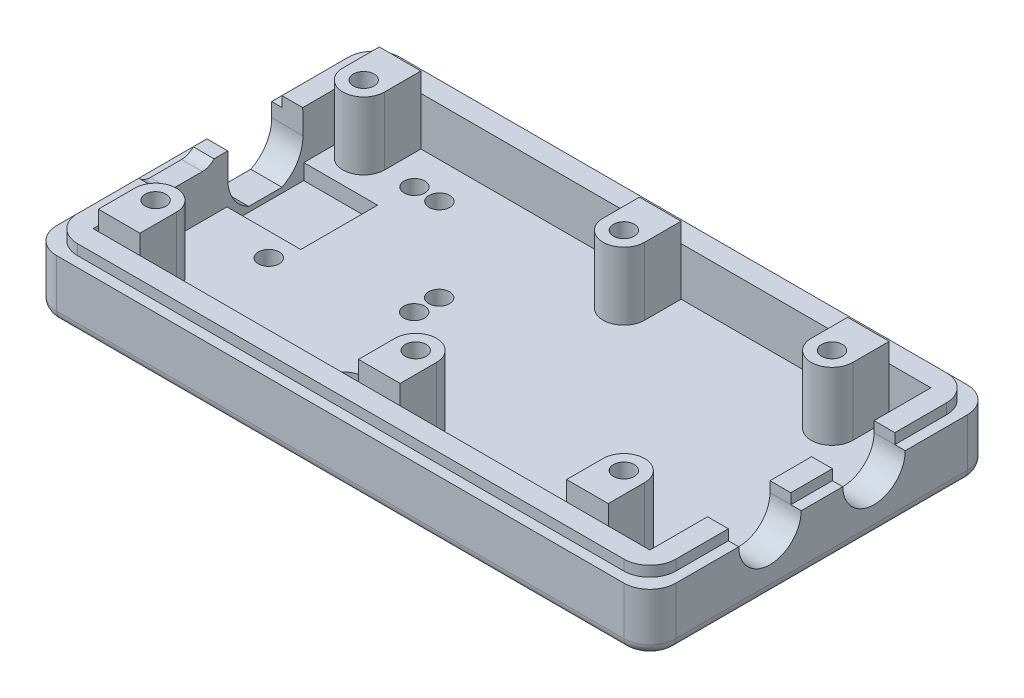
from build123d import *

# Parameters (mm, degrees)
SKETCH1_W           = 107
SKETCH1_H           = 54
BOSS_EXTRUDE1_DEPTH = 9.25
BOSS_EXTRUDE2_START = -4
BOSS_EXTRUDE2_DEPTH = 4
FILLET1_R           = 2
SKETCH2_R           = 2
BOSS_EXTRUDE3_DEPTH = 12.9838
SKETCH3_R           = 2
SKETCH3_R_2         = 3
CUT_EXTRUDE1_DEPTH  = 14
CUT_EXTRUDE2_DEPTH  = 6
CUT_EXTRUDE3_DEPTH  = 6
SKETCH7_W           = 14.17999989
SKETCH7_H           = 14.7574
CUT_EXTRUDE4_DEPTH  = 3
SKETCH8_OUTSIDE_W   = 148.426
SKETCH8_OUTSIDE_H   = 95.426
CUT_EXTRUDE5_DEPTH  = 2
CUT_EXTRUDE6_REACH  = 124.256
SKETCH11_W          = 0.217094017
SKETCH11_H          = 0.814102564
SKETCH11_W_2        = 1.546794872
SKETCH11_H_2        = 0.189957265
CUT_EXTRUDE7_DEPTH  = 1.5


with BuildPart() as part:
    # Sketch1 → Boss-Extrude1 (new body)
    with BuildSketch(Plane(origin=(0, 0, 0), x_dir=(1, 0, 0), z_dir=(0, 1, 0))):
        with BuildLine():
            Line((-54.5, -33), (54.5, -33))
            ThreePointArc((54.5, -33), (58.035533906, -31.535533906), (59.5, -28))
            Line((59.5, -28), (59.5, 28))
            ThreePointArc((59.5, 28), (58.035533906, 31.535533906), (54.5, 33))
            Line((54.5, 33), (-54.5, 33))
            ThreePointArc((-54.5, 33), (-58.035533906, 31.535533906), (-59.5, 28))
            Line((-59.5, 28), (-59.5, -28))
            ThreePointArc((-59.5, -28), (-58.035533906, -31.535533906), (-54.5, -33))
        make_face()
        Rectangle(SKETCH1_W, SKETCH1_H, mode=Mode.SUBTRACT)
    extrude(amount=BOSS_EXTRUDE1_DEPTH)

    # Sketch1<2> → Boss-Extrude2 (add)
    with BuildSketch(Plane(origin=(0, 0, 0), x_dir=(1, 0, 0), z_dir=(0, 1, 0)).offset(BOSS_EXTRUDE2_START)):
        with BuildLine():
            Line((-54.5, -33), (54.5, -33))
            ThreePointArc((54.5, -33), (58.035533906, -31.535533906), (59.5, -28))
            Line((59.5, -28), (59.5, 28))
            ThreePointArc((59.5, 28), (58.035533906, 31.535533906), (54.5, 33))
            Line((54.5, 33), (-54.5, 33))
            ThreePointArc((-54.5, 33), (-58.035533906, 31.535533906), (-59.5, 28))
            Line((-59.5, 28), (-59.5, -28))
            ThreePointArc((-59.5, -28), (-58.035533906, -31.535533906), (-54.5, -33))
        make_face()
    extrude(amount=BOSS_EXTRUDE2_DEPTH)

    # Fillet1
    fillet1_edges = [part.edges().sort_by_distance(p)[0] for p in [
        (0, -4, 33),
        (59.5, -4, 0),
        (58.035533906, -4, 31.535533906),
        (-58.035533906, -4, 31.535533906),
        (-59.5, -4, 0),
        (-58.035533906, -4, -31.535533906),
        (0, -4, -33),
        (58.035533906, -4, -31.535533906),
    ]]
    fillet(fillet1_edges, radius=FILLET1_R)

    # Sketch2 → Boss-Extrude3 (add)
    # profile 1 of 6: a face of its own
    with BuildSketch(Plane(origin=(0, 0, 0), x_dir=(1, 0, 0), z_dir=(0, 1, 0))):
        with BuildLine():
            Line((-52.5, 27), (-52.5, 20))
            ThreePointArc((-52.5, 20), (-48.5, 16), (-44.5, 20))
            Line((-44.5, 20), (-44.5, 27))
            Line((-44.5, 27), (-52.5, 27))
        make_face()
        with Locations(Location((-48.5, 20, 0), (0, 0, 90))):
            Circle(SKETCH2_R, mode=Mode.SUBTRACT)
    # profile 2 of 6: a face of its own
    with BuildSketch(Plane(origin=(0, 0, 0), x_dir=(1, 0, 0), z_dir=(0, 1, 0))):
        with BuildLine():
            Line((-2.5, 27), (-2.5, 20))
            ThreePointArc((-2.5, 20), (1.5, 16), (5.5, 20))
            Line((5.5, 20), (5.5, 27))
            Line((5.5, 27), (-2.5, 27))
        make_face()
        with Locations(Location((1.5, 20, 0), (0, 0, 90))):
            Circle(SKETCH2_R, mode=Mode.SUBTRACT)
    # profile 3 of 6: a face of its own
    with BuildSketch(Plane(origin=(0, 0, 0), x_dir=(1, 0, 0), z_dir=(0, 1, 0))):
        with BuildLine():
            Line((37.5, 27), (37.5, 20))
            ThreePointArc((37.5, 20), (41.5, 16), (45.5, 20))
            Line((45.5, 20), (45.5, 27))
            Line((45.5, 27), (37.5, 27))
        make_face()
        with Locations(Location((41.5, 20, 0), (0, 0, 90))):
            Circle(SKETCH2_R, mode=Mode.SUBTRACT)
    # profile 4 of 6: a face of its own
    with BuildSketch(Plane(origin=(0, 0, 0), x_dir=(1, 0, 0), z_dir=(0, 1, 0))):
        with BuildLine():
            Line((5.5, -27), (-2.5, -27))
            Line((-2.5, -27), (-2.5, -20))
            ThreePointArc((-2.5, -20), (1.5, -16), (5.5, -20))
            Line((5.5, -20), (5.5, -27))
        make_face()
        with Locations(Location((1.5, -20, 0), (0, 0, 90))):
            Circle(SKETCH2_R, mode=Mode.SUBTRACT)
    # profile 5 of 6: a face of its own
    with BuildSketch(Plane(origin=(0, 0, 0), x_dir=(1, 0, 0), z_dir=(0, 1, 0))):
        with BuildLine():
            Line((45.5, -27), (37.5, -27))
            Line((37.5, -27), (37.5, -20))
            ThreePointArc((37.5, -20), (41.5, -16), (45.5, -20))
            Line((45.5, -20), (45.5, -27))
        make_face()
        with Locations(Location((41.5, -20, 0), (0, 0, 90))):
            Circle(SKETCH2_R, mode=Mode.SUBTRACT)
    # profile 6 of 6: a face of its own
    with BuildSketch(Plane(origin=(0, 0, 0), x_dir=(1, 0, 0), z_dir=(0, 1, 0))):
        with BuildLine():
            Line((-52.5, -27), (-44.5, -27))
            Line((-44.5, -27), (-44.5, -20))
            ThreePointArc((-44.5, -20), (-48.5, -16), (-52.5, -20))
            Line((-52.5, -20), (-52.5, -27))
        make_face()
        with Locations(Location((-48.5, -20, 0), (0, 0, 90))):
            Circle(SKETCH2_R, mode=Mode.SUBTRACT)
    extrude(amount=BOSS_EXTRUDE3_DEPTH)

    # Sketch3 → Cut-Extrude1 (cut)
    with BuildSketch(Plane(origin=(0, 0, 0), x_dir=(1, 0, 0), z_dir=(0, 1, 0))):
        with Locations(Location((-18, 4, 0), (0, 0, 270))):
            Circle(SKETCH3_R)
        with Locations(Location((-18, -0.8, 0), (0, 0, 270))):
            Circle(SKETCH3_R)
        with Locations(Location((-41, -5.75, 0), (0, 0, 270))):
            Circle(SKETCH3_R)
        with Locations(Location((-34, 20.05, 0), (0, 0, 270))):
            Circle(SKETCH3_R)
        with Locations(Location((-38.8, 20.05, 0), (0, 0, 270))):
            Circle(SKETCH3_R)
        with Locations(Location((-12.500000098, -9.500000015, 0), (0, 0, 270))):
            Circle(SKETCH3_R_2)
        with Locations(Location((-12.500000098, -19.500000015, 0), (0, 0, 270))):
            Circle(SKETCH3_R_2)
    extrude(amount=-CUT_EXTRUDE1_DEPTH, mode=Mode.SUBTRACT)

    # Sketch4 → Cut-Extrude2 (cut)
    with BuildSketch(Plane(origin=(59.5, 0, 0), x_dir=(0, 0, -1), z_dir=(1, 0, 0))):
        with BuildLine():
            Line((-15.920000153, 7.26879997), (-15.920000153, 9.25))
            Line((-15.920000153, 9.25), (-3.920000153, 9.25))
            Line((-3.920000153, 9.25), (-3.920000153, 7.26879997))
            ThreePointArc((-3.920000153, 7.26879997), (-9.920000153, 1.26879997), (-15.920000153, 7.26879997))
        make_face()
        with BuildLine():
            Line((4.079999847, 7.26879997), (4.079999847, 9.25))
            Line((4.079999847, 9.25), (16.079999847, 9.25))
            Line((16.079999847, 9.25), (16.079999847, 7.26879997))
            ThreePointArc((16.079999847, 7.26879997), (10.079999847, 1.26879997), (4.079999847, 7.26879997))
        make_face()
    extrude(amount=-CUT_EXTRUDE2_DEPTH, mode=Mode.SUBTRACT)

    # Sketch6 → Cut-Extrude3 (cut)
    with BuildSketch(Plane.ZY.offset(59.5)):
        with BuildLine():
            Line((-9.28511199, -2.017600179), (-2.91488801, -2.017600179))
            ThreePointArc((-2.91488801, -2.017600179), (0.033296759, 0.647675089), (1.126224696, 4.468799821))
            Line((1.126224696, 4.468799821), (1.126224696, 9.25))
            Line((1.126224696, 9.25), (-13.232213, 14.5))
            Line((-13.232213, 14.5), (-13.325905205, 4.536750644))
            ThreePointArc((-13.325905205, 4.536750644), (-12.251194879, 0.676554456), (-9.28511199, -2.017600179))
        make_face()
    extrude(amount=-CUT_EXTRUDE3_DEPTH, mode=Mode.SUBTRACT)

    # Sketch7 → Cut-Extrude4 (cut)
    with BuildSketch(Plane(origin=(0, 0, 0), x_dir=(1, 0, 0), z_dir=(0, 1, 0))):
        with Locations((-46.410000055, 6.1)):
            Rectangle(SKETCH7_W, SKETCH7_H)
    extrude(amount=-CUT_EXTRUDE4_DEPTH, mode=Mode.SUBTRACT)

    # Sketch8 outside → Cut-Extrude5 (cut)
    with BuildSketch(Plane(origin=(0, 9.25, 0), x_dir=(1, 0, 0), z_dir=(0, 1, 0))):
        Rectangle(SKETCH8_OUTSIDE_W, SKETCH8_OUTSIDE_H)
        with BuildLine():
            Line((-52.5, -31), (52.5, -31))
            ThreePointArc((52.5, -31), (56.035533906, -29.535533906), (57.5, -26))
            Line((57.5, -26), (57.5, 26))
            ThreePointArc((57.5, 26), (56.035533906, 29.535533906), (52.5, 31))
            Line((52.5, 31), (-52.5, 31))
            ThreePointArc((-52.5, 31), (-56.035533906, 29.535533906), (-57.5, 26))
            Line((-57.5, 26), (-57.5, -26))
            ThreePointArc((-57.5, -26), (-56.035533906, -29.535533906), (-52.5, -31))
        make_face(mode=Mode.SUBTRACT)
    extrude(amount=-CUT_EXTRUDE5_DEPTH, mode=Mode.SUBTRACT)

    # Sketch10 → Cut-Extrude6 (cut, up to next)
    with BuildSketch(Plane.ZY.offset(57.5), mode=Mode.PRIVATE) as cut_extrude6_sk1:
        with BuildLine():
            Line((3, 13.331262071), (15, 13.331262071))
            Line((15, 13.331262071), (15, 11.25))
            ThreePointArc((15, 11.25), (14.121320344, 9.128679656), (12, 8.25))
            Line((12, 8.25), (6, 8.25))
            ThreePointArc((6, 8.25), (3.878679656, 9.128679656), (3, 11.25))
            Line((3, 11.25), (3, 13.331262071))
        make_face()
    cut_extrude6_tool1 = extrude(cut_extrude6_sk1.sketch, amount=-CUT_EXTRUDE6_REACH, mode=Mode.PRIVATE) & part.part
    add(cut_extrude6_tool1.solids().sort_by_distance((-57.5, 10.917146, 9))[0], mode=Mode.SUBTRACT)

    # Sketch11 → Cut-Extrude7 (cut)
    # profile 1 of 48: a face of its own
    with BuildSketch(Plane.XZ.offset(4)):
        with BuildLine():
            Line((-28.511538462, -28.144704861), (-28.600156918, -28.313461538))
            add(Edge.make_bspline(
                [(-28.600156918, -28.313461538), (-28.624008791, -28.300011758), (-28.67041509, -28.273843812), (-28.734203136, -28.228875719), (-28.791390093, -28.181679521), (-28.841090676, -28.130627444), (-28.884181641, -28.076348267), (-28.92163439, -28.018762257), (-28.953901638, -27.958061839), (-28.9809425, -27.894033039), (-29.001758615, -27.82612267), (-29.016455033, -27.75414183), (-29.025541052, -27.677959394), (-29.026596374, -27.625740468), (-29.027136752, -27.599001736)],
                knots=[0, 0, 0, 0, 1.120373846, 2.179803828, 3.190307243, 4.151866639, 5.090753574, 6.023181945, 6.960194942, 7.901556876, 8.864247182, 9.862852693, 10.905672442, 12, 12, 12, 12], degree=3))
            add(Edge.make_bspline(
                [(-29.027136752, -27.599001736), (-29.026442984, -27.56928254), (-29.025089644, -27.511308999), (-29.013422297, -27.426920674), (-28.994389011, -27.347467413), (-28.967800336, -27.272953645), (-28.933070443, -27.203561987), (-28.890761741, -27.139154011), (-28.8410908, -27.079392923), (-28.783630305, -27.026154693), (-28.72213014, -26.978247862), (-28.658076604, -26.935898483), (-28.591437124, -26.900740413), (-28.523248068, -26.871174125), (-28.4528819, -26.848772816), (-28.380724275, -26.832375017), (-28.306417645, -26.823102752), (-28.256166304, -26.821664807), (-28.230842682, -26.820940171)],
                knots=[0, 0, 0, 0, 1.145226127, 2.234004399, 3.276654467, 4.290038057, 5.276870678, 6.260645262, 7.254731018, 8.264593254, 9.273837991, 10.257612574, 11.220387342, 12.174754112, 13.118989047, 14.062768009, 15.023752772, 16, 16, 16, 16], degree=3))
            add(Edge.make_bspline(
                [(-28.230842682, -26.820940171), (-28.207078665, -26.821580699), (-28.159981523, -26.822850142), (-28.090273312, -26.830851618), (-28.022522772, -26.845032252), (-27.956673606, -26.864491267), (-27.892836068, -26.889619878), (-27.830971305, -26.920361268), (-27.771145149, -26.956763325), (-27.733406111, -26.984868228), (-27.714396368, -26.999025107)],
                knots=[0, 0, 0, 0, 1.024358464, 2.0301432, 3.019427413, 4.004406732, 4.986367066, 5.972626655, 6.978780325, 8, 8, 8, 8], degree=3))
            add(Edge.make_bspline(
                [(-27.714396368, -26.999025107), (-27.691494718, -27.018200705), (-27.646416884, -27.055944468), (-27.587187515, -27.119780931), (-27.537570565, -27.188905335), (-27.49644244, -27.262451414), (-27.465192187, -27.341273948), (-27.441904268, -27.424313377), (-27.428854709, -27.512515231), (-27.427011496, -27.572813151), (-27.426068376, -27.603665865)],
                knots=[0, 0, 0, 0, 1.030682036, 2.02871468, 2.997146059, 3.962720338, 4.930598197, 5.918074684, 6.934738563, 8, 8, 8, 8], degree=3))
            add(Edge.make_bspline(
                [(-27.426068376, -27.603665865), (-27.426887253, -27.635384179), (-27.428493704, -27.69760828), (-27.443386772, -27.788341991), (-27.467004269, -27.874194425), (-27.500359181, -27.955131225), (-27.543393767, -28.031160598), (-27.596698595, -28.101788352), (-27.658637152, -28.168222362), (-27.706270141, -28.206871836), (-27.730508814, -28.226539129)],
                knots=[0, 0, 0, 0, 1.056321875, 2.072262726, 3.055038591, 4.01806755, 4.982017516, 5.957941055, 6.960871419, 8, 8, 8, 8], degree=3))
            add(Edge.make_bspline(
                [(-27.730508814, -28.226539129), (-27.74877479, -28.239920659), (-27.785185157, -28.266594646), (-27.844555332, -28.300005987), (-27.906670787, -28.329008793), (-27.972535586, -28.352191107), (-28.041369332, -28.370962615), (-28.113664109, -28.384543644), (-28.189398389, -28.392508127), (-28.241000639, -28.394073673), (-28.267307692, -28.394871795)],
                knots=[0, 0, 0, 0, 0.94817472, 1.890038105, 2.849395472, 3.817997239, 4.812318967, 5.836947057, 6.897266129, 8, 8, 8, 8], degree=3))
            Line((-28.267307692, -28.394871795), (-28.267307692, -27.010897436))
            add(Edge.make_bspline(
                [(-28.267307692, -27.010897436), (-28.287688037, -27.011829415), (-28.327765163, -27.013662116), (-28.386415258, -27.022185849), (-28.442257904, -27.035686601), (-28.495055172, -27.054453038), (-28.54498041, -27.077984214), (-28.5923777, -27.105903285), (-28.636527222, -27.139415023), (-28.678001098, -27.17673161), (-28.714921476, -27.218288734), (-28.747992543, -27.261992824), (-28.775557372, -27.308417508), (-28.79826867, -27.357094782), (-28.815748807, -27.408277092), (-28.827786223, -27.461892462), (-28.835827823, -27.517774104), (-28.836723501, -27.555865092), (-28.837179487, -27.575257078)],
                knots=[0, 0, 0, 0, 1.094405546, 2.152104367, 3.174987145, 4.173015398, 5.153654967, 6.133208507, 7.119289451, 8.123438607, 9.122504012, 10.097966803, 11.060604936, 12.014205423, 12.976096155, 13.956823727, 14.959826266, 16, 16, 16, 16], degree=3))
            add(Edge.make_bspline(
                [(-28.837179487, -27.575257078), (-28.836814315, -27.594217541), (-28.836089744, -27.631838736), (-28.828939546, -27.687994824), (-28.81756724, -27.743272558), (-28.801936497, -27.797274908), (-28.782681343, -27.848827722), (-28.759600603, -27.896707455), (-28.734360851, -27.941075408), (-28.705039554, -27.982303698), (-28.669521531, -28.022293573), (-28.624690467, -28.061463914), (-28.57221351, -28.10403158), (-28.532556366, -28.130615591), (-28.511538462, -28.144704861)],
                knots=[0, 0, 0, 0, 0.990963276, 1.966261236, 2.95471375, 3.93937425, 4.902926125, 5.828461241, 6.715766441, 7.568835615, 8.469155523, 9.505141836, 10.677749234, 12, 12, 12, 12], degree=3))
        make_face()
        with BuildLine():
            add(Edge.make_bspline(
                [(-28.077350427, -28.20491453), (-28.052148219, -28.197973666), (-28.003642081, -28.184614738), (-27.936631278, -28.156521276), (-27.876730808, -28.125601588), (-27.824929714, -28.088281168), (-27.779243808, -28.045631194), (-27.738915359, -27.996888317), (-27.703009967, -27.942167265), (-27.672671676, -27.881844948), (-27.646856679, -27.817954551), (-27.62954471, -27.751064747), (-27.617685761, -27.682812496), (-27.616581379, -27.636648449), (-27.616025641, -27.613418136)],
                knots=[0, 0, 0, 0, 1.154756201, 2.222533969, 3.206705588, 4.129403772, 5.035894089, 5.963342549, 6.920206228, 7.923656548, 8.944970878, 9.96070521, 10.973801891, 12, 12, 12, 12], degree=3))
            add(Edge.make_bspline(
                [(-27.616025641, -27.613418136), (-27.616397118, -27.594459714), (-27.61713145, -27.556982901), (-27.624045589, -27.50175991), (-27.6356232, -27.448630337), (-27.651041568, -27.397301647), (-27.672284955, -27.348667273), (-27.696688523, -27.301461578), (-27.726670689, -27.256850599), (-27.749502906, -27.228944932), (-27.76103766, -27.214847089)],
                knots=[0, 0, 0, 0, 1.048700258, 2.073059931, 3.073189922, 4.055269162, 5.032885305, 6.005420607, 6.992345662, 8, 8, 8, 8], degree=3))
            add(Edge.make_bspline(
                [(-27.76103766, -27.214847089), (-27.770166127, -27.204751628), (-27.78863992, -27.184320875), (-27.820468059, -27.157021607), (-27.854789242, -27.130883512), (-27.892916532, -27.107096017), (-27.934415765, -27.085277667), (-27.978936906, -27.064860919), (-28.026817799, -27.046484375), (-28.060183988, -27.036145299), (-28.077350427, -27.030825988)],
                knots=[0, 0, 0, 0, 0.879870761, 1.780643979, 2.707998968, 3.669668524, 4.684282772, 5.740141944, 6.837334558, 8, 8, 8, 8], degree=3))
            Line((-28.077350427, -27.030825988), (-28.077350427, -28.20491453))
        make_face(mode=Mode.SUBTRACT)
    # profile 2 of 48: a face of its own
    with BuildSketch(Plane.XZ.offset(4)):
        with BuildLine():
            Line((-27.453205128, -26.251068376), (-27.453205128, -26.441025641))
            Line((-27.453205128, -26.441025641), (-28.680719151, -26.441025641))
            add(Edge.make_bspline(
                [(-28.680719151, -26.441025641), (-28.706867601, -26.440858096), (-28.757340408, -26.440534694), (-28.830322034, -26.438205774), (-28.897732476, -26.433294697), (-28.959879176, -26.427725638), (-29.016474071, -26.419714528), (-29.067686037, -26.409931678), (-29.11356422, -26.398903434), (-29.141821624, -26.389215016), (-29.155188301, -26.384632078)],
                knots=[0, 0, 0, 0, 1.307562039, 2.523909702, 3.650326591, 4.686913197, 5.643429486, 6.506965704, 7.293745905, 8, 8, 8, 8], degree=3))
            add(Edge.make_bspline(
                [(-29.155188301, -26.384632078), (-29.172563668, -26.377865908), (-29.20679489, -26.364535872), (-29.255308868, -26.339558487), (-29.301028627, -26.311632848), (-29.343431759, -26.279625066), (-29.383185416, -26.244344895), (-29.419595416, -26.205144489), (-29.453226844, -26.162720867), (-29.483414313, -26.116728788), (-29.509866518, -26.06763418), (-29.533279649, -26.016089997), (-29.553500743, -25.962245247), (-29.568678271, -25.905582011), (-29.58182027, -25.846960993), (-29.590375089, -25.785700531), (-29.596196987, -25.722156405), (-29.596735391, -25.678948975), (-29.597008547, -25.657027911)],
                knots=[0, 0, 0, 0, 0.981884813, 1.934411902, 2.870642727, 3.801527012, 4.729816098, 5.667674509, 6.616731011, 7.579249157, 8.562291171, 9.552107921, 10.560574871, 11.588648803, 12.640348669, 13.724070705, 14.845319185, 16, 16, 16, 16], degree=3))
            add(Edge.make_bspline(
                [(-29.597008547, -25.657027911), (-29.596491725, -25.625044921), (-29.595482233, -25.562573547), (-29.583678862, -25.471497817), (-29.567097775, -25.385112756), (-29.541736816, -25.304511566), (-29.51083027, -25.230005731), (-29.475628313, -25.161929597), (-29.4348575, -25.101402825), (-29.388610079, -25.046890272), (-29.333593908, -24.997700538), (-29.268765581, -24.951418975), (-29.193129448, -24.906871879), (-29.137616778, -24.880765097), (-29.108547009, -24.867094017)],
                knots=[0, 0, 0, 0, 1.157931887, 2.261752077, 3.322178827, 4.340878186, 5.316509817, 6.24181319, 7.112369066, 7.954886437, 8.824930176, 9.778504873, 10.836691706, 12, 12, 12, 12], degree=3))
            Line((-29.108547009, -24.867094017), (-29.108547009, -25.057051282))
            add(Edge.make_bspline(
                [(-29.108547009, -25.057051282), (-29.132801514, -25.072328904), (-29.180216087, -25.102194773), (-29.241607376, -25.158043616), (-29.294072506, -25.219249347), (-29.336351879, -25.287877537), (-29.368228753, -25.364213738), (-29.390952861, -25.448303877), (-29.404557746, -25.54083222), (-29.406197433, -25.605250378), (-29.407051282, -25.638795406)],
                knots=[0, 0, 0, 0, 0.997731894, 1.950442991, 2.880492273, 3.800895997, 4.748200782, 5.754801363, 6.83083817, 8, 8, 8, 8], degree=3))
            add(Edge.make_bspline(
                [(-29.407051282, -25.638795406), (-29.406190314, -25.671917198), (-29.404530455, -25.735772696), (-29.390885656, -25.827718039), (-29.368285816, -25.911701898), (-29.336525957, -25.987093464), (-29.297300315, -26.052753832), (-29.253901848, -26.10955391), (-29.204789554, -26.15559304), (-29.159568285, -26.186567042), (-29.119276011, -26.205819084), (-29.08459147, -26.218079034), (-29.045370882, -26.228041841), (-29.001745948, -26.236375369), (-28.953654276, -26.243252062), (-28.900985924, -26.247608091), (-28.843860584, -26.250756367), (-28.804252829, -26.250961968), (-28.783754006, -26.251068376)],
                knots=[0, 0, 0, 0, 1.570672572, 3.028099501, 4.397683431, 5.686589315, 6.895122698, 8.017723291, 9.066023084, 10.075791025, 10.603605416, 11.180458235, 11.81795017, 12.521450677, 13.286658401, 14.121327423, 15.027701111, 16, 16, 16, 16], degree=3))
            Line((-28.783754006, -26.251068376), (-28.703615785, -26.251068376))
            add(Edge.make_bspline(
                [(-28.703615785, -26.251068376), (-28.726561542, -26.231787891), (-28.772049446, -26.193566058), (-28.831655769, -26.127557913), (-28.882991667, -26.055460064), (-28.925094365, -25.977395255), (-28.958768369, -25.895275699), (-28.982319589, -25.809990826), (-28.997535338, -25.722305154), (-28.999172619, -25.662885997), (-29, -25.632859241)],
                knots=[0, 0, 0, 0, 1.012485704, 2.007162095, 2.997754123, 3.998611389, 4.999708251, 5.992315798, 6.98544096, 8, 8, 8, 8], degree=3))
            add(Edge.make_bspline(
                [(-29, -25.632859241), (-28.999688532, -25.615178259), (-28.999069281, -25.580025532), (-28.993651353, -25.52780147), (-28.985790209, -25.476348062), (-28.974250482, -25.425785308), (-28.959438819, -25.376040247), (-28.940922981, -25.327195085), (-28.919989079, -25.278854328), (-28.895331229, -25.231896704), (-28.867897877, -25.186789782), (-28.838180391, -25.143874209), (-28.806335238, -25.103373245), (-28.772044975, -25.065677984), (-28.735371808, -25.030817206), (-28.696660107, -24.998398864), (-28.65560535, -24.968716034), (-28.612191557, -24.942153411), (-28.567477206, -24.917885824), (-28.521248118, -24.897108368), (-28.473796755, -24.879860407), (-28.425716333, -24.864659651), (-28.376130087, -24.853895637), (-28.325625715, -24.845664844), (-28.273895101, -24.841046837), (-28.239048593, -24.840321994), (-28.221514423, -24.839957265)],
                knots=[0, 0, 0, 0, 1.028796061, 2.045417375, 3.052978994, 4.056772505, 5.061374657, 6.071351207, 7.095367434, 8.125609542, 9.155490328, 10.16637099, 11.162041966, 12.151987513, 13.129482149, 14.104793677, 15.088808581, 16.075021637, 17.065069715, 18.0481558, 19.021557435, 20.00254184, 20.980451754, 21.971763498, 22.979425854, 24, 24, 24, 24], degree=3))
            add(Edge.make_bspline(
                [(-28.221514423, -24.839957265), (-28.203974372, -24.840271017), (-28.168962204, -24.840897307), (-28.117026869, -24.846313779), (-28.065781081, -24.85402332), (-28.01578085, -24.866289446), (-27.966304348, -24.880844044), (-27.918157084, -24.899720759), (-27.870701875, -24.921469142), (-27.824354874, -24.946326506), (-27.779542476, -24.974151665), (-27.737182487, -25.004779665), (-27.69692256, -25.037570229), (-27.659279069, -25.073183256), (-27.623969861, -25.11140823), (-27.591304777, -25.152356268), (-27.560693388, -25.195571925), (-27.532807541, -25.241203218), (-27.508143849, -25.288542227), (-27.485639126, -25.336387296), (-27.467778006, -25.385371931), (-27.452040229, -25.434582946), (-27.440891325, -25.484886989), (-27.432290255, -25.53566727), (-27.427050162, -25.587097636), (-27.42639606, -25.621540577), (-27.426068376, -25.638795406)],
                knots=[0, 0, 0, 0, 1.008914434, 2.013921196, 3.001938835, 3.98818112, 4.973517748, 5.967241793, 6.960633033, 7.975722852, 8.991170928, 9.993245185, 10.981396684, 11.976616977, 12.972235889, 13.973022409, 14.988340224, 16.01763096, 17.047082309, 18.058647952, 19.057085865, 20.044802253, 21.029198803, 22.0185208, 23.007341325, 24, 24, 24, 24], degree=3))
            add(Edge.make_bspline(
                [(-27.426068376, -25.638795406), (-27.426876056, -25.667252318), (-27.428467006, -25.723306137), (-27.441337857, -25.805961907), (-27.461398495, -25.885807274), (-27.490560413, -25.96325126), (-27.530024548, -26.038766575), (-27.582674456, -26.111898739), (-27.647470164, -26.183899721), (-27.697659217, -26.22810869), (-27.723724626, -26.251068376)],
                knots=[0, 0, 0, 0, 0.967343326, 1.905452219, 2.838102277, 3.762990896, 4.713322225, 5.726933809, 6.819495538, 8, 8, 8, 8], degree=3))
            Line((-27.723724626, -26.251068376), (-27.453205128, -26.251068376))
        make_face()
        with BuildLine():
            add(Edge.make_bspline(
                [(-27.616025641, -25.654059829), (-27.616969706, -25.626282677), (-27.618838753, -25.571289807), (-27.634795344, -25.490682267), (-27.659799311, -25.41286271), (-27.69556825, -25.339322842), (-27.73916168, -25.270427067), (-27.792005193, -25.209334069), (-27.852181452, -25.155798612), (-27.91971735, -25.111073405), (-27.99224563, -25.075135799), (-28.068596579, -25.049008215), (-28.147890457, -25.032682622), (-28.201932499, -25.030841613), (-28.229146635, -25.02991453)],
                knots=[0, 0, 0, 0, 1.026331696, 2.03191913, 3.02692423, 4.041490544, 5.047661868, 6.033509946, 7.018359977, 8.017132933, 9.01989117, 10.003339456, 10.994534818, 12, 12, 12, 12], degree=3))
            add(Edge.make_bspline(
                [(-28.229146635, -25.02991453), (-28.249668309, -25.03035324), (-28.29002844, -25.031216054), (-28.349255787, -25.039518406), (-28.405674584, -25.052922204), (-28.459250518, -25.071971736), (-28.510496891, -25.095420737), (-28.558466187, -25.125623872), (-28.604038548, -25.160384605), (-28.646277397, -25.200257132), (-28.684805257, -25.244125788), (-28.718481928, -25.291677362), (-28.746404096, -25.342651431), (-28.770178243, -25.396233495), (-28.787667573, -25.453557955), (-28.800988954, -25.513765228), (-28.808616141, -25.57725916), (-28.809560999, -25.620543167), (-28.810042735, -25.642611512)],
                knots=[0, 0, 0, 0, 1.039892369, 2.045164194, 3.025377528, 3.974939947, 4.923826224, 5.876304068, 6.842270891, 7.825700405, 8.815919897, 9.798017152, 10.773083594, 11.758208475, 12.764450271, 13.80592145, 14.881349344, 16, 16, 16, 16], degree=3))
            add(Edge.make_bspline(
                [(-28.810042735, -25.642611512), (-28.809578514, -25.664965785), (-28.808670736, -25.708679329), (-28.800867191, -25.772524607), (-28.788274855, -25.833020604), (-28.770396254, -25.890111813), (-28.747583611, -25.944013923), (-28.718714196, -25.994120941), (-28.685837134, -26.041509043), (-28.647486185, -26.084658537), (-28.605229012, -26.123695698), (-28.559215603, -26.157645171), (-28.510333962, -26.186802389), (-28.457960874, -26.210008587), (-28.402788414, -26.229150967), (-28.343886264, -26.241219077), (-28.282121358, -26.249874352), (-28.239779622, -26.250664318), (-28.218122329, -26.251068376)],
                knots=[0, 0, 0, 0, 1.121992135, 2.194043731, 3.223932285, 4.220423016, 5.193184374, 6.156086365, 7.118779155, 8.084057622, 9.048292205, 10.002025119, 10.950065319, 11.899697616, 12.87359713, 13.875731462, 14.913461982, 16, 16, 16, 16], degree=3))
            add(Edge.make_bspline(
                [(-28.218122329, -26.251068376), (-28.189929626, -26.250258256), (-28.134850993, -26.248675567), (-28.054595001, -26.233739665), (-27.979139638, -26.209657926), (-27.908723677, -26.175883912), (-27.844092742, -26.133561554), (-27.78644563, -26.08258531), (-27.735701363, -26.023836412), (-27.693445903, -25.957475571), (-27.659178548, -25.885983019), (-27.633809, -25.811207208), (-27.619103801, -25.733359008), (-27.617059408, -25.680691604), (-27.616025641, -25.654059829)],
                knots=[0, 0, 0, 0, 1.070930318, 2.092221514, 3.091405799, 4.074392322, 5.052047932, 6.019043127, 6.99061078, 7.993717296, 9.000730765, 9.998165278, 10.987753177, 12, 12, 12, 12], degree=3))
        make_face(mode=Mode.SUBTRACT)
    # profile 3 of 48: a face of its own
    with BuildSketch(Plane.XZ.offset(4)):
        with BuildLine():
            Line((-27.453205128, -23.103205128), (-27.453205128, -23.293162393))
            Line((-27.453205128, -23.293162393), (-27.732204861, -23.293162393))
            add(Edge.make_bspline(
                [(-27.732204861, -23.293162393), (-27.706899976, -23.313444677), (-27.657794965, -23.352803157), (-27.593254427, -23.418349873), (-27.540068505, -23.48762166), (-27.497672401, -23.560194301), (-27.465712775, -23.636166311), (-27.442631473, -23.715074599), (-27.428791601, -23.797391587), (-27.426983224, -23.853371033), (-27.426068376, -23.881690705)],
                knots=[0, 0, 0, 0, 1.12780773, 2.188550248, 3.19190651, 4.159438251, 5.104880172, 6.052711206, 7.014878035, 8, 8, 8, 8], degree=3))
            add(Edge.make_bspline(
                [(-27.426068376, -23.881690705), (-27.427125374, -23.910313696), (-27.429194174, -23.966335794), (-27.445510706, -24.047915809), (-27.473542101, -24.12417668), (-27.511552037, -24.194951346), (-27.559074364, -24.258613423), (-27.614735232, -24.314016712), (-27.678267966, -24.360231341), (-27.737389402, -24.391170768), (-27.789812295, -24.411570028), (-27.834714648, -24.42440977), (-27.884739207, -24.435314455), (-27.939736076, -24.444767869), (-28.000090198, -24.451164525), (-28.065554285, -24.456209618), (-28.136107095, -24.459825307), (-28.184903294, -24.45996876), (-28.210066106, -24.460042735)],
                knots=[0, 0, 0, 0, 1.235764744, 2.418689688, 3.575570385, 4.733739044, 5.876600945, 6.994686206, 8.113221397, 9.257403329, 9.866223892, 10.540462211, 11.272173464, 12.077110251, 12.949508505, 13.892531187, 14.913238277, 16, 16, 16, 16], degree=3))
            Line((-28.210066106, -24.460042735), (-29, -24.460042735))
            Line((-29, -24.460042735), (-29, -24.27008547))
            Line((-29, -24.27008547), (-28.272395833, -24.27008547))
            add(Edge.make_bspline(
                [(-28.272395833, -24.27008547), (-28.251336545, -24.269968625), (-28.211053711, -24.269745121), (-28.153378159, -24.269040182), (-28.101074371, -24.267340918), (-28.054267392, -24.264953129), (-28.013002167, -24.261458191), (-27.977194652, -24.257815933), (-27.946890309, -24.253361876), (-27.928647617, -24.249392876), (-27.920466079, -24.247612847)],
                knots=[0, 0, 0, 0, 1.430800155, 2.736877192, 3.918605307, 4.986035426, 5.920637409, 6.731861385, 7.431261377, 8, 8, 8, 8], degree=3))
            add(Edge.make_bspline(
                [(-27.920466079, -24.247612847), (-27.896450267, -24.241186931), (-27.85022726, -24.228819029), (-27.787528961, -24.198258001), (-27.734190057, -24.159665616), (-27.690540325, -24.112555964), (-27.656570343, -24.057384094), (-27.63300038, -23.994303108), (-27.618258541, -23.92392174), (-27.616790704, -23.874419327), (-27.616025641, -23.848617788)],
                knots=[0, 0, 0, 0, 1.084156227, 2.086665306, 3.027808233, 3.945421172, 4.874247719, 5.839848303, 6.874090471, 8, 8, 8, 8], degree=3))
            add(Edge.make_bspline(
                [(-27.616025641, -23.848617788), (-27.616313403, -23.833336802), (-27.616882877, -23.803096126), (-27.622600225, -23.758253828), (-27.631943058, -23.714753907), (-27.644585193, -23.672177218), (-27.661788474, -23.631426928), (-27.681701505, -23.591312204), (-27.70608571, -23.552981058), (-27.733408545, -23.515708514), (-27.763859127, -23.481072999), (-27.795519748, -23.44838383), (-27.829723332, -23.419662865), (-27.865258698, -23.393592118), (-27.902840168, -23.371114582), (-27.942065888, -23.35148646), (-27.982997939, -23.334834384), (-28.011406604, -23.32655955), (-28.025620994, -23.322419204)],
                knots=[0, 0, 0, 0, 1.02388931, 2.02625049, 3.024079426, 4.004119353, 4.998163158, 5.985366248, 7.002659681, 8.039138713, 9.080111048, 10.09169763, 11.086418407, 12.069932368, 13.043171485, 14.017654831, 15.008125612, 16, 16, 16, 16], degree=3))
            add(Edge.make_bspline(
                [(-28.025620994, -23.322419204), (-28.036056283, -23.320036655), (-28.058773362, -23.314849969), (-28.096053559, -23.309247951), (-28.139179115, -23.30416337), (-28.188099707, -23.299907685), (-28.242986612, -23.297303933), (-28.303605428, -23.294464941), (-28.370197871, -23.293431366), (-28.416559943, -23.293254561), (-28.440728499, -23.293162393)],
                knots=[0, 0, 0, 0, 0.615963638, 1.340920617, 2.168419149, 3.115676021, 4.16674242, 5.331190069, 6.6087489, 8, 8, 8, 8], degree=3))
            Line((-28.440728499, -23.293162393), (-29, -23.293162393))
            Line((-29, -23.293162393), (-29, -23.103205128))
            Line((-29, -23.103205128), (-27.453205128, -23.103205128))
        make_face()
    # profile 4 of 48: a face of its own
    with BuildSketch(Plane.XZ.offset(4)):
        with BuildLine():
            Line((-27.453205128, -22.669017094), (-29, -22.669017094))
            Line((-29, -22.669017094), (-29, -22.479059829))
            Line((-29, -22.479059829), (-28.732448584, -22.479059829))
            add(Edge.make_bspline(
                [(-28.732448584, -22.479059829), (-28.756669541, -22.457644373), (-28.803937043, -22.415851841), (-28.865504081, -22.346062325), (-28.916812779, -22.272393183), (-28.957868141, -22.194595298), (-28.988942246, -22.112901439), (-29.010794458, -22.027544577), (-29.025019651, -21.938638471), (-29.026424721, -21.878007573), (-29.027136752, -21.847282318)],
                knots=[0, 0, 0, 0, 1.074295371, 2.096500925, 3.086030275, 4.053105238, 5.014108356, 5.985331429, 6.979048527, 8, 8, 8, 8], degree=3))
            add(Edge.make_bspline(
                [(-29.027136752, -21.847282318), (-29.026395212, -21.819966386), (-29.024932862, -21.766098159), (-29.013584366, -21.686857832), (-28.995369048, -21.610598102), (-28.970004935, -21.537270366), (-28.936533915, -21.467371481), (-28.896029358, -21.400507585), (-28.84826733, -21.336522629), (-28.793452536, -21.276633473), (-28.733978844, -21.221414187), (-28.670360045, -21.173102889), (-28.603469942, -21.132157491), (-28.533327334, -21.098507707), (-28.459983495, -21.07246774), (-28.383488742, -21.054350969), (-28.303970357, -21.043014702), (-28.249820033, -21.041553093), (-28.222362447, -21.040811966)],
                knots=[0, 0, 0, 0, 1.034036272, 2.039165313, 3.024406509, 3.999331371, 4.971254918, 5.953351348, 6.95522652, 7.989525907, 9.023492927, 10.024309745, 11.009187477, 11.988246066, 12.964946762, 13.950187958, 14.960617622, 16, 16, 16, 16], degree=3))
            add(Edge.make_bspline(
                [(-28.222362447, -21.040811966), (-28.195472378, -21.041569531), (-28.142312163, -21.043067195), (-28.064130987, -21.054229667), (-27.988820972, -21.072986192), (-27.916661093, -21.099358751), (-27.847360738, -21.133026429), (-27.781462115, -21.174675995), (-27.71795716, -21.222969884), (-27.658882365, -21.278779324), (-27.60451229, -21.339206007), (-27.556634191, -21.403548953), (-27.516233484, -21.471005869), (-27.483391637, -21.541712016), (-27.457293506, -21.615166732), (-27.439100596, -21.691928014), (-27.428406077, -21.771646781), (-27.426855097, -21.825766653), (-27.426068376, -21.853218483)],
                knots=[0, 0, 0, 0, 1.02050356, 2.017480486, 2.990790918, 3.96161403, 4.928589988, 5.909588639, 6.91611943, 7.952353252, 8.989586576, 9.99823133, 10.991940466, 11.968822692, 12.952985106, 13.945868367, 14.958059758, 16, 16, 16, 16], degree=3))
            add(Edge.make_bspline(
                [(-27.426068376, -21.853218483), (-27.42693364, -21.884788198), (-27.428630381, -21.946694919), (-27.442900838, -22.037362267), (-27.466713397, -22.123213154), (-27.499440558, -22.204742436), (-27.542607956, -22.281633842), (-27.597553361, -22.352941042), (-27.663021545, -22.420099567), (-27.713454132, -22.459024289), (-27.739413061, -22.479059829)],
                knots=[0, 0, 0, 0, 1.03879612, 2.037030165, 3.012306674, 3.966139504, 4.922386257, 5.905048148, 6.921675258, 8, 8, 8, 8], degree=3))
            Line((-27.739413061, -22.479059829), (-27.453205128, -22.479059829))
            Line((-27.453205128, -22.479059829), (-27.453205128, -22.669017094))
        make_face()
        with BuildLine():
            add(Edge.make_bspline(
                [(-27.616025641, -21.855762553), (-27.617013592, -21.827995294), (-27.618963651, -21.773187141), (-27.634187776, -21.692727439), (-27.659517405, -21.615732228), (-27.69416149, -21.542592066), (-27.737713666, -21.474441952), (-27.790431168, -21.41359311), (-27.850637562, -21.359317545), (-27.918839031, -21.314443444), (-27.991120506, -21.276610112), (-28.067252758, -21.25066584), (-28.145123657, -21.233401679), (-28.197960679, -21.231648998), (-28.224482505, -21.230769231)],
                knots=[0, 0, 0, 0, 1.031093775, 2.03521511, 3.029845951, 4.035119871, 5.034286494, 6.024708811, 7.017619509, 8.03559408, 9.050082311, 10.039808432, 11.016071318, 12, 12, 12, 12], degree=3))
            add(Edge.make_bspline(
                [(-28.224482505, -21.230769231), (-28.250840612, -21.231907444), (-28.30345351, -21.234179408), (-28.381555774, -21.250210769), (-28.457381538, -21.277987684), (-28.53066427, -21.314957465), (-28.599005731, -21.360838127), (-28.660389454, -21.41466324), (-28.713318375, -21.476288017), (-28.757619899, -21.544585953), (-28.79328052, -21.61742056), (-28.81842637, -21.694050933), (-28.83430462, -21.773130655), (-28.836217975, -21.82699714), (-28.837179487, -21.854066506)],
                knots=[0, 0, 0, 0, 0.979154363, 1.954470772, 2.947816011, 3.971783346, 4.997163654, 5.998045606, 6.995988793, 8.00538986, 9.015323546, 10.000094788, 10.994993517, 12, 12, 12, 12], degree=3))
            add(Edge.make_bspline(
                [(-28.837179487, -21.854066506), (-28.836190639, -21.881554086), (-28.834228919, -21.936085113), (-28.818750188, -22.016734189), (-28.793735499, -22.095120363), (-28.75859556, -22.170077615), (-28.715244759, -22.239854107), (-28.664270042, -22.302399858), (-28.6054835, -22.355806867), (-28.540357094, -22.400578753), (-28.469294591, -22.4359463), (-28.393312428, -22.460891488), (-28.313007716, -22.476212494), (-28.258048285, -22.478097594), (-28.229994658, -22.479059829)],
                knots=[0, 0, 0, 0, 1.017484689, 2.018529338, 3.030031036, 4.058138743, 5.076350332, 6.065651025, 7.036469986, 8.00785331, 8.984076697, 9.96571663, 10.961615403, 12, 12, 12, 12], degree=3))
            add(Edge.make_bspline(
                [(-28.229994658, -22.479059829), (-28.208623693, -22.478479456), (-28.16655887, -22.477337099), (-28.10479592, -22.468610171), (-28.045690717, -22.454727426), (-27.989178568, -22.435167441), (-27.935581325, -22.409463839), (-27.88447886, -22.378495611), (-27.836347185, -22.341627555), (-27.791247254, -22.299981658), (-27.750317365, -22.253882454), (-27.714242105, -22.204861925), (-27.683712507, -22.153043406), (-27.659280844, -22.098463272), (-27.639376981, -22.041541901), (-27.626230823, -21.981733714), (-27.617175149, -21.919641467), (-27.616412845, -21.877279717), (-27.616025641, -21.855762553)],
                knots=[0, 0, 0, 0, 1.050062701, 2.066855696, 3.059271411, 4.030305351, 4.999747758, 5.975466543, 6.961907836, 7.974539719, 8.98812422, 9.98710676, 10.961662635, 11.93785114, 12.922015094, 13.919620009, 14.94329489, 16, 16, 16, 16], degree=3))
        make_face(mode=Mode.SUBTRACT)
    # profile 5 of 48: a face of its own
    with BuildSketch(Plane.XZ.offset(4)):
        with BuildLine():
            Line((-27.453205128, -20.145299145), (-27.453205128, -20.33525641))
            Line((-27.453205128, -20.33525641), (-27.680899439, -20.33525641))
            add(Edge.make_bspline(
                [(-27.680899439, -20.33525641), (-27.659696792, -20.349278403), (-27.619146893, -20.376095356), (-27.565551857, -20.420695988), (-27.520978727, -20.466366725), (-27.485862743, -20.513675542), (-27.459348579, -20.562226954), (-27.439764638, -20.611213625), (-27.428380981, -20.661650328), (-27.426840277, -20.695611927), (-27.426068376, -20.71262687)],
                knots=[0, 0, 0, 0, 1.280622107, 2.44917983, 3.507334186, 4.490567186, 5.408878616, 6.288712897, 7.142636019, 8, 8, 8, 8], degree=3))
            add(Edge.make_bspline(
                [(-27.426068376, -20.71262687), (-27.426772254, -20.725830877), (-27.428213198, -20.752861457), (-27.438843944, -20.793904298), (-27.455172499, -20.836365365), (-27.470903272, -20.863766339), (-27.479069845, -20.877991453)],
                knots=[0, 0, 0, 0, 0.90119973, 1.844890732, 2.881183062, 4, 4, 4, 4], degree=3))
            Line((-27.479069845, -20.877991453), (-27.643586405, -20.773684562))
            add(Edge.make_bspline(
                [(-27.643586405, -20.773684562), (-27.639510149, -20.764547202), (-27.631772634, -20.747202742), (-27.622615323, -20.721830219), (-27.617223317, -20.69843722), (-27.616406455, -20.683533735), (-27.616025641, -20.676585871)],
                knots=[0, 0, 0, 0, 1.180555205, 2.24091978, 3.179933427, 4, 4, 4, 4], degree=3))
            add(Edge.make_bspline(
                [(-27.616025641, -20.676585871), (-27.617004306, -20.661189225), (-27.618982668, -20.630065036), (-27.635644023, -20.5844356), (-27.661431279, -20.53995786), (-27.691048198, -20.505084289), (-27.719060686, -20.477875336), (-27.743656383, -20.458448029), (-27.771216877, -20.440615176), (-27.801292581, -20.423579718), (-27.83439079, -20.408057482), (-27.870182634, -20.39357068), (-27.908709043, -20.380472205), (-27.935549904, -20.373003251), (-27.949298878, -20.36917735)],
                knots=[0, 0, 0, 0, 1.135927944, 2.296268816, 3.551388088, 4.924624343, 5.663947748, 6.437790805, 7.238014523, 8.089896346, 8.992356783, 9.939655789, 10.944608424, 12, 12, 12, 12], degree=3))
            add(Edge.make_bspline(
                [(-27.949298878, -20.36917735), (-27.96156174, -20.366315379), (-27.988723048, -20.35997633), (-28.034290965, -20.353812877), (-28.088129083, -20.347723216), (-28.15038726, -20.343431451), (-28.220910024, -20.339453302), (-28.29980481, -20.337209586), (-28.387152599, -20.335332924), (-28.448218041, -20.335282689), (-28.480161592, -20.33525641)],
                knots=[0, 0, 0, 0, 0.566838948, 1.255505196, 2.06880316, 3.007127437, 4.065329342, 5.249902469, 6.561414163, 8, 8, 8, 8], degree=3))
            Line((-28.480161592, -20.33525641), (-29, -20.33525641))
            Line((-29, -20.33525641), (-29, -20.145299145))
            Line((-29, -20.145299145), (-27.453205128, -20.145299145))
        make_face()
    # profile 6 of 48: a face of its own
    with BuildSketch(Plane.XZ.offset(4)):
        with Locations((-28.185897436, -19.494017094)):
            Rectangle(SKETCH11_W, SKETCH11_H)
    # profile 7 of 48: a face of its own
    with BuildSketch(Plane.XZ.offset(4)):
        with BuildLine():
            Line((-27.453205128, -18.272863248), (-27.453205128, -18.462820513))
            Line((-27.453205128, -18.462820513), (-27.680899439, -18.462820513))
            add(Edge.make_bspline(
                [(-27.680899439, -18.462820513), (-27.659696792, -18.476842506), (-27.619146893, -18.503659459), (-27.565551857, -18.54826009), (-27.520978727, -18.593930828), (-27.485862743, -18.641239645), (-27.459348579, -18.689791057), (-27.439764638, -18.738777727), (-27.428380981, -18.789214431), (-27.426840277, -18.82317603), (-27.426068376, -18.840190972)],
                knots=[0, 0, 0, 0, 1.280622107, 2.44917983, 3.507334186, 4.490567186, 5.408878616, 6.288712897, 7.142636019, 8, 8, 8, 8], degree=3))
            add(Edge.make_bspline(
                [(-27.426068376, -18.840190972), (-27.426772254, -18.85339498), (-27.428213198, -18.88042556), (-27.438843944, -18.9214684), (-27.455172499, -18.963929468), (-27.470903272, -18.991330442), (-27.479069845, -19.005555556)],
                knots=[0, 0, 0, 0, 0.90119973, 1.844890732, 2.881183062, 4, 4, 4, 4], degree=3))
            Line((-27.479069845, -19.005555556), (-27.643586405, -18.901248665))
            add(Edge.make_bspline(
                [(-27.643586405, -18.901248665), (-27.639510149, -18.892111304), (-27.631772634, -18.874766845), (-27.622615323, -18.849394321), (-27.617223317, -18.826001323), (-27.616406455, -18.811097837), (-27.616025641, -18.804149973)],
                knots=[0, 0, 0, 0, 1.180555205, 2.24091978, 3.179933427, 4, 4, 4, 4], degree=3))
            add(Edge.make_bspline(
                [(-27.616025641, -18.804149973), (-27.617004306, -18.788753328), (-27.618982668, -18.757629138), (-27.635644023, -18.711999702), (-27.661431279, -18.667521963), (-27.691048198, -18.632648392), (-27.719060686, -18.605439439), (-27.743656383, -18.586012131), (-27.771216877, -18.568179279), (-27.801292581, -18.551143821), (-27.83439079, -18.535621585), (-27.870182634, -18.521134783), (-27.908709043, -18.508036308), (-27.935549904, -18.500567353), (-27.949298878, -18.496741453)],
                knots=[0, 0, 0, 0, 1.135927944, 2.296268816, 3.551388088, 4.924624343, 5.663947748, 6.437790805, 7.238014523, 8.089896346, 8.992356783, 9.939655789, 10.944608424, 12, 12, 12, 12], degree=3))
            add(Edge.make_bspline(
                [(-27.949298878, -18.496741453), (-27.96156174, -18.493879482), (-27.988723048, -18.487540433), (-28.034290965, -18.481376979), (-28.088129083, -18.475287318), (-28.15038726, -18.470995554), (-28.220910024, -18.467017405), (-28.29980481, -18.464773688), (-28.387152599, -18.462897027), (-28.448218041, -18.462846791), (-28.480161592, -18.462820513)],
                knots=[0, 0, 0, 0, 0.566838948, 1.255505196, 2.06880316, 3.007127437, 4.065329342, 5.249902469, 6.561414163, 8, 8, 8, 8], degree=3))
            Line((-28.480161592, -18.462820513), (-29, -18.462820513))
            Line((-29, -18.462820513), (-29, -18.272863248))
            Line((-29, -18.272863248), (-27.453205128, -18.272863248))
        make_face()
    # profile 8 of 48: a face of its own
    with BuildSketch(Plane.XZ.offset(4)):
        with BuildLine():
            Line((-28.511538462, -17.697055288), (-28.600156918, -17.865811966))
            add(Edge.make_bspline(
                [(-28.600156918, -17.865811966), (-28.624008791, -17.852362186), (-28.67041509, -17.826194239), (-28.734203136, -17.781226146), (-28.791390093, -17.734029948), (-28.841090676, -17.682977871), (-28.884181641, -17.628698695), (-28.92163439, -17.571112684), (-28.953901638, -17.510412266), (-28.9809425, -17.446383467), (-29.001758615, -17.378473098), (-29.016455033, -17.306492257), (-29.025541052, -17.230309822), (-29.026596374, -17.178090896), (-29.027136752, -17.151352163)],
                knots=[0, 0, 0, 0, 1.120373846, 2.179803828, 3.190307243, 4.151866639, 5.090753574, 6.023181945, 6.960194942, 7.901556876, 8.864247182, 9.862852693, 10.905672442, 12, 12, 12, 12], degree=3))
            add(Edge.make_bspline(
                [(-29.027136752, -17.151352163), (-29.026442984, -17.121632968), (-29.025089644, -17.063659426), (-29.013422297, -16.979271101), (-28.994389011, -16.899817841), (-28.967800336, -16.825304073), (-28.933070443, -16.755912414), (-28.890761741, -16.691504439), (-28.8410908, -16.63174335), (-28.783630305, -16.57850512), (-28.72213014, -16.530598289), (-28.658076604, -16.48824891), (-28.591437124, -16.45309084), (-28.523248068, -16.423524552), (-28.4528819, -16.401123243), (-28.380724275, -16.384725444), (-28.306417645, -16.375453179), (-28.256166304, -16.374015235), (-28.230842682, -16.373290598)],
                knots=[0, 0, 0, 0, 1.145226127, 2.234004399, 3.276654467, 4.290038057, 5.276870678, 6.260645262, 7.254731018, 8.264593254, 9.273837991, 10.257612574, 11.220387342, 12.174754112, 13.118989047, 14.062768009, 15.023752772, 16, 16, 16, 16], degree=3))
            add(Edge.make_bspline(
                [(-28.230842682, -16.373290598), (-28.207078665, -16.373931127), (-28.159981523, -16.375200569), (-28.090273312, -16.383202045), (-28.022522772, -16.39738268), (-27.956673606, -16.416841695), (-27.892836068, -16.441970305), (-27.830971305, -16.472711695), (-27.771145149, -16.509113752), (-27.733406111, -16.537218655), (-27.714396368, -16.551375534)],
                knots=[0, 0, 0, 0, 1.024358464, 2.0301432, 3.019427413, 4.004406732, 4.986367066, 5.972626655, 6.978780325, 8, 8, 8, 8], degree=3))
            add(Edge.make_bspline(
                [(-27.714396368, -16.551375534), (-27.691494718, -16.570551133), (-27.646416884, -16.608294896), (-27.587187515, -16.672131358), (-27.537570565, -16.741255763), (-27.49644244, -16.814801841), (-27.465192187, -16.893624376), (-27.441904268, -16.976663804), (-27.428854709, -17.064865659), (-27.427011496, -17.125163578), (-27.426068376, -17.156016293)],
                knots=[0, 0, 0, 0, 1.030682036, 2.02871468, 2.997146059, 3.962720338, 4.930598197, 5.918074684, 6.934738563, 8, 8, 8, 8], degree=3))
            add(Edge.make_bspline(
                [(-27.426068376, -17.156016293), (-27.426887253, -17.187734606), (-27.428493704, -17.249958708), (-27.443386772, -17.340692419), (-27.467004269, -17.426544852), (-27.500359181, -17.507481652), (-27.543393767, -17.583511025), (-27.596698595, -17.654138779), (-27.658637152, -17.720572789), (-27.706270141, -17.759222263), (-27.730508814, -17.778889557)],
                knots=[0, 0, 0, 0, 1.056321875, 2.072262726, 3.055038591, 4.01806755, 4.982017516, 5.957941055, 6.960871419, 8, 8, 8, 8], degree=3))
            add(Edge.make_bspline(
                [(-27.730508814, -17.778889557), (-27.74877479, -17.792271086), (-27.785185157, -17.818945073), (-27.844555332, -17.852356415), (-27.906670787, -17.88135922), (-27.972535586, -17.904541535), (-28.041369332, -17.923313043), (-28.113664109, -17.936894071), (-28.189398389, -17.944858555), (-28.241000639, -17.9464241), (-28.267307692, -17.947222222)],
                knots=[0, 0, 0, 0, 0.94817472, 1.890038105, 2.849395472, 3.817997239, 4.812318967, 5.836947057, 6.897266129, 8, 8, 8, 8], degree=3))
            Line((-28.267307692, -17.947222222), (-28.267307692, -16.563247863))
            add(Edge.make_bspline(
                [(-28.267307692, -16.563247863), (-28.287688037, -16.564179843), (-28.327765163, -16.566012543), (-28.386415258, -16.574536276), (-28.442257904, -16.588037028), (-28.495055172, -16.606803465), (-28.54498041, -16.630334641), (-28.5923777, -16.658253712), (-28.636527222, -16.69176545), (-28.678001098, -16.729082038), (-28.714921476, -16.770639161), (-28.747992543, -16.814343252), (-28.775557372, -16.860767935), (-28.79826867, -16.90944521), (-28.815748807, -16.96062752), (-28.827786223, -17.014242889), (-28.835827823, -17.070124531), (-28.836723501, -17.108215519), (-28.837179487, -17.127607505)],
                knots=[0, 0, 0, 0, 1.094405546, 2.152104367, 3.174987145, 4.173015398, 5.153654967, 6.133208507, 7.119289451, 8.123438607, 9.122504012, 10.097966803, 11.060604936, 12.014205423, 12.976096155, 13.956823727, 14.959826266, 16, 16, 16, 16], degree=3))
            add(Edge.make_bspline(
                [(-28.837179487, -17.127607505), (-28.836814315, -17.146567968), (-28.836089744, -17.184189163), (-28.828939546, -17.240345251), (-28.81756724, -17.295622986), (-28.801936497, -17.349625335), (-28.782681343, -17.401178149), (-28.759600603, -17.449057882), (-28.734360851, -17.493425836), (-28.705039554, -17.534654125), (-28.669521531, -17.574644001), (-28.624690467, -17.613814341), (-28.57221351, -17.656382008), (-28.532556366, -17.682966019), (-28.511538462, -17.697055288)],
                knots=[0, 0, 0, 0, 0.990963276, 1.966261236, 2.95471375, 3.93937425, 4.902926125, 5.828461241, 6.715766441, 7.568835615, 8.469155523, 9.505141836, 10.677749234, 12, 12, 12, 12], degree=3))
        make_face()
        with BuildLine():
            add(Edge.make_bspline(
                [(-28.077350427, -17.757264957), (-28.052148219, -17.750324094), (-28.003642081, -17.736965166), (-27.936631278, -17.708871703), (-27.876730808, -17.677952015), (-27.824929714, -17.640631595), (-27.779243808, -17.597981621), (-27.738915359, -17.549238744), (-27.703009967, -17.494517692), (-27.672671676, -17.434195375), (-27.646856679, -17.370304978), (-27.62954471, -17.303415174), (-27.617685761, -17.235162924), (-27.616581379, -17.188998877), (-27.616025641, -17.165768563)],
                knots=[0, 0, 0, 0, 1.154756201, 2.222533969, 3.206705588, 4.129403772, 5.035894089, 5.963342549, 6.920206228, 7.923656548, 8.944970878, 9.96070521, 10.973801891, 12, 12, 12, 12], degree=3))
            add(Edge.make_bspline(
                [(-27.616025641, -17.165768563), (-27.616397118, -17.146810142), (-27.61713145, -17.109333329), (-27.624045589, -17.054110337), (-27.6356232, -17.000980764), (-27.651041568, -16.949652075), (-27.672284955, -16.9010177), (-27.696688523, -16.853812006), (-27.726670689, -16.809201027), (-27.749502906, -16.781295359), (-27.76103766, -16.767197516)],
                knots=[0, 0, 0, 0, 1.048700258, 2.073059931, 3.073189922, 4.055269162, 5.032885305, 6.005420607, 6.992345662, 8, 8, 8, 8], degree=3))
            add(Edge.make_bspline(
                [(-27.76103766, -16.767197516), (-27.770166127, -16.757102055), (-27.78863992, -16.736671302), (-27.820468059, -16.709372035), (-27.854789242, -16.683233939), (-27.892916532, -16.659446445), (-27.934415765, -16.637628095), (-27.978936906, -16.617211347), (-28.026817799, -16.598834802), (-28.060183988, -16.588495726), (-28.077350427, -16.583176416)],
                knots=[0, 0, 0, 0, 0.879870761, 1.780643979, 2.707998968, 3.669668524, 4.684282772, 5.740141944, 6.837334558, 8, 8, 8, 8], degree=3))
            Line((-28.077350427, -16.583176416), (-28.077350427, -17.757264957))
        make_face(mode=Mode.SUBTRACT)
    # profile 9 of 48: a face of its own
    with BuildSketch(Plane.XZ.offset(4)):
        Polygon((-27.453205128, -14.636538462), (-27.453205128, -14.842184161), (-28.579380342, -15.355662393), (-27.453205128, -15.869140625), (-27.453205128, -16.074786325), (-29, -15.369230769), (-29, -15.342094017), align=None)
    # profile 10 of 48: a face of its own
    with BuildSketch(Plane.XZ.offset(4)):
        with BuildLine():
            add(Edge.make_bspline(
                [(-26.829059829, -13.293269231), (-26.830052542, -13.332462696), (-26.832002313, -13.409441897), (-26.846927166, -13.52257778), (-26.872748182, -13.63058488), (-26.90713503, -13.734345461), (-26.953015218, -13.832609492), (-27.008439117, -13.926149937), (-27.074194984, -14.014702321), (-27.149179466, -14.097454955), (-27.231063038, -14.172903465), (-27.31869948, -14.238822309), (-27.410888746, -14.294556194), (-27.507951632, -14.340237351), (-27.609460929, -14.376107057), (-27.7159938, -14.400851109), (-27.826850254, -14.416659075), (-27.902461801, -14.418507009), (-27.940818643, -14.419444444)],
                knots=[0, 0, 0, 0, 1.06508495, 2.091914715, 3.094501328, 4.079693967, 5.057647778, 6.035986298, 7.030177474, 8.050107388, 9.066943579, 10.051896531, 11.025616101, 11.9896488, 12.96281505, 13.945825876, 14.957941789, 16, 16, 16, 16], degree=3))
            add(Edge.make_bspline(
                [(-27.940818643, -14.419444444), (-27.978892941, -14.418507148), (-28.053941793, -14.416659629), (-28.164094739, -14.400833118), (-28.26998465, -14.376015404), (-28.371424477, -14.340570088), (-28.468559369, -14.295108383), (-28.560918088, -14.238997819), (-28.649161333, -14.1735154), (-28.731442413, -14.098327671), (-28.807039141, -14.016463625), (-28.873060471, -13.928580056), (-28.929480573, -13.836481517), (-28.974848407, -13.739477308), (-29.010971972, -13.638648864), (-29.03562419, -13.533072096), (-29.0515198, -13.423218098), (-29.05334553, -13.348305783), (-29.054273504, -13.310229701)],
                knots=[0, 0, 0, 0, 1.04355943, 2.056976533, 3.044937463, 4.02179873, 4.997890911, 5.980248884, 6.980147982, 8.006253959, 9.032111064, 10.031228745, 11.015595249, 11.988180414, 12.962670953, 13.946861971, 14.95644057, 16, 16, 16, 16], degree=3))
            add(Edge.make_bspline(
                [(-29.054273504, -13.310229701), (-29.05333662, -13.271873014), (-29.051489771, -13.196261774), (-29.035654452, -13.085266642), (-29.010901323, -12.978656634), (-28.975492857, -12.876760001), (-28.929903847, -12.779543304), (-28.873881723, -12.687015945), (-28.807867344, -12.599066739), (-28.732779717, -12.516590671), (-28.650876329, -12.441218693), (-28.563570422, -12.374924687), (-28.471692325, -12.319225543), (-28.375620778, -12.273617287), (-28.275604108, -12.237542893), (-28.171013173, -12.21292389), (-28.062434054, -12.196997528), (-27.98850627, -12.195162083), (-27.950994925, -12.194230769)],
                knots=[0, 0, 0, 0, 1.053167129, 2.076072758, 3.073341244, 4.055601477, 5.033424535, 6.017524495, 7.021518915, 8.049444456, 9.077120685, 10.074910483, 11.055688766, 12.022980584, 12.991883888, 13.970269434, 14.970104079, 16, 16, 16, 16], degree=3))
            add(Edge.make_bspline(
                [(-27.950994925, -12.194230769), (-27.925816958, -12.1945538), (-27.875778654, -12.195195786), (-27.801475308, -12.202936077), (-27.728358898, -12.214145137), (-27.656675206, -12.230293508), (-27.586412526, -12.251123536), (-27.517714549, -12.276793012), (-27.450015407, -12.306210242), (-27.384603532, -12.341235517), (-27.321376258, -12.37944914), (-27.261124188, -12.421117257), (-27.204923587, -12.466530397), (-27.151871401, -12.515039844), (-27.102873112, -12.567317077), (-27.056860442, -12.622575326), (-27.014309699, -12.681103727), (-26.976114565, -12.742994844), (-26.941031871, -12.806670739), (-26.911740708, -12.872593384), (-26.885851248, -12.939371878), (-26.865276804, -13.007594432), (-26.84890354, -13.077103236), (-26.83777832, -13.147985184), (-26.830020831, -13.220167267), (-26.829381541, -13.268797069), (-26.829059829, -13.293269231)],
                knots=[0, 0, 0, 0, 1.037115869, 2.061148057, 3.07517727, 4.084041727, 5.086514338, 6.092668487, 7.104487461, 8.125783165, 9.147610153, 10.147694368, 11.141876323, 12.122903372, 13.107606018, 14.091946891, 15.084523921, 16.086505767, 17.087268121, 18.077809654, 19.05670789, 20.036870126, 21.011670792, 21.99694167, 22.991993299, 24, 24, 24, 24], degree=3))
        make_face()
        with BuildLine():
            add(Edge.make_bspline(
                [(-27.046153846, -13.302597489), (-27.046398592, -13.282510498), (-27.046885743, -13.24252855), (-27.053307447, -13.183090484), (-27.062450938, -13.124430905), (-27.075526831, -13.066553004), (-27.093178813, -13.009768245), (-27.113977908, -12.953509554), (-27.13844489, -12.898047067), (-27.166974002, -12.844000813), (-27.198138957, -12.791461133), (-27.232343577, -12.741544065), (-27.269422003, -12.694747566), (-27.308884455, -12.65092173), (-27.351132447, -12.610194265), (-27.3954917, -12.571739598), (-27.443239202, -12.537105423), (-27.493077767, -12.505364068), (-27.544943134, -12.476959729), (-27.59828909, -12.451701628), (-27.653550836, -12.431040538), (-27.710128826, -12.414190434), (-27.767933457, -12.400220548), (-27.827403232, -12.391370509), (-27.888239323, -12.384879986), (-27.929352159, -12.384420461), (-27.950146902, -12.384188034)],
                knots=[0, 0, 0, 0, 1.008585988, 2.007529826, 2.999688727, 3.990042337, 4.984966365, 5.984641633, 7.001812546, 8.027570247, 9.052811818, 10.068991095, 11.064725446, 12.050001529, 13.029093193, 14.010961114, 14.996492974, 15.989185205, 16.977398719, 17.96520407, 18.951579521, 19.937648295, 20.929603947, 21.935788061, 22.955928099, 24, 24, 24, 24], degree=3))
            add(Edge.make_bspline(
                [(-27.950146902, -12.384188034), (-27.980725007, -12.384959022), (-28.040881599, -12.386475794), (-28.129036619, -12.399754896), (-28.213756678, -12.420209138), (-28.294578214, -12.450360973), (-28.372195947, -12.48806825), (-28.445921324, -12.534651179), (-28.515774272, -12.589841197), (-28.581267125, -12.652532949), (-28.641045302, -12.721066205), (-28.693516506, -12.793838856), (-28.737912229, -12.870071276), (-28.774080058, -12.94996226), (-28.802739566, -13.033085296), (-28.822381405, -13.119976005), (-28.835308466, -13.210055569), (-28.836549895, -13.271457441), (-28.837179487, -13.302597489)],
                knots=[0, 0, 0, 0, 1.032063989, 2.030389145, 3.003944642, 3.970395727, 4.937377036, 5.913328081, 6.909231446, 7.93887556, 8.970685674, 9.976071282, 10.964166581, 11.944589148, 12.933237628, 13.927779006, 14.949070134, 16, 16, 16, 16], degree=3))
            add(Edge.make_bspline(
                [(-28.837179487, -13.302597489), (-28.836891921, -13.323527998), (-28.836321591, -13.365039483), (-28.830577141, -13.426782957), (-28.821365533, -13.487414127), (-28.808102536, -13.546847756), (-28.791504148, -13.605017115), (-28.771781864, -13.662162301), (-28.747188356, -13.717684701), (-28.719971846, -13.772246683), (-28.689168018, -13.824482857), (-28.655441512, -13.874042293), (-28.619026192, -13.920637674), (-28.579906427, -13.964369925), (-28.538419437, -14.005379585), (-28.493498526, -14.042553072), (-28.446455589, -14.077602158), (-28.396500775, -14.109216417), (-28.344526114, -14.137564284), (-28.29097809, -14.162214513), (-28.236040729, -14.183139964), (-28.179620921, -14.200029241), (-28.121829527, -14.213264956), (-28.062588168, -14.222384657), (-28.002015626, -14.228763967), (-27.961046721, -14.229244797), (-27.940394631, -14.229487179)],
                knots=[0, 0, 0, 0, 1.047226202, 2.076964084, 3.100341814, 4.114585567, 5.122123135, 6.126552355, 7.137064942, 8.158803602, 9.176592812, 10.169297945, 11.156925011, 12.133779169, 13.104132798, 14.073170763, 15.049307625, 16.038276215, 17.028988595, 18.010110019, 18.986169996, 19.968539974, 20.955178716, 21.950601663, 22.966915103, 24, 24, 24, 24], degree=3))
            add(Edge.make_bspline(
                [(-27.940394631, -14.229487179), (-27.919883826, -14.229244602), (-27.879196867, -14.228763404), (-27.819046753, -14.222387717), (-27.760231715, -14.213255274), (-27.702982653, -14.200094017), (-27.647284974, -14.183130352), (-27.593190988, -14.162213253), (-27.540499175, -14.137547857), (-27.489339767, -14.109240026), (-27.440248378, -14.077419981), (-27.393317395, -14.042649652), (-27.349428165, -14.004328704), (-27.307497189, -13.963552011), (-27.268418729, -13.919301054), (-27.232179955, -13.871776242), (-27.197905799, -13.821554681), (-27.166988228, -13.768379289), (-27.138430286, -13.713502111), (-27.113983899, -13.657185517), (-27.09308886, -13.599968828), (-27.075599084, -13.542144989), (-27.062438127, -13.483306655), (-27.053310728, -13.423796468), (-27.046885056, -13.363512707), (-27.046398356, -13.322966997), (-27.046153846, -13.302597489)],
                knots=[0, 0, 0, 0, 1.029967493, 2.04313025, 3.035375922, 4.01889446, 4.991458755, 5.958017022, 6.930036849, 7.912118993, 8.892942568, 9.867138445, 10.843712051, 11.817804417, 12.803729339, 13.806387533, 14.818654169, 15.856205545, 16.894655496, 17.924916651, 18.938004761, 19.953404357, 20.957695443, 21.963967554, 22.97713031, 24, 24, 24, 24], degree=3))
        make_face(mode=Mode.SUBTRACT)
    # profile 11 of 48: a face of its own
    with BuildSketch(Plane.XZ.offset(4)):
        Polygon((-5.953205226, 27.662179487), (-5.953205226, 27.436181223), (-6.511204692, 27.038034188), (-5.953205226, 26.639887153), (-5.953205226, 26.413888889), (-6.669361076, 26.92482305), (-7.500000098, 26.332478632), (-7.500000098, 26.558476896), (-6.827941471, 27.038034188), (-7.500000098, 27.51759148), (-7.500000098, 27.743589744), (-6.669361076, 27.150821314), align=None)
    # profile 12 of 48: a face of its own
    with BuildSketch(Plane.XZ.offset(4)):
        Polygon((-5.383333431, 25.801191907), (-5.383333431, 25.40982906), (-7.500000098, 25.40982906), (-7.500000098, 25.599786325), (-5.600427448, 25.599786325), (-5.600427448, 25.92542735), align=None)
    # profile 13 of 48: a face of its own
    with BuildSketch(Plane.XZ.offset(4)):
        with BuildLine():
            add(Edge.make_bspline(
                [(-6.442514788, 24.622863248), (-6.408589225, 24.622664875), (-6.34268833, 24.622279533), (-6.246661427, 24.617992726), (-6.156575919, 24.610871448), (-6.072427495, 24.601112178), (-5.994194423, 24.589235881), (-5.9220858, 24.573381736), (-5.855767794, 24.555352147), (-5.795024449, 24.534455947), (-5.739036362, 24.510878295), (-5.686771876, 24.485213283), (-5.638297346, 24.456456374), (-5.592884553, 24.426201973), (-5.551040328, 24.393344505), (-5.512843911, 24.358230536), (-5.478272241, 24.320511747), (-5.446913855, 24.280934132), (-5.419596703, 24.239247571), (-5.394982134, 24.196737121), (-5.374779451, 24.152652652), (-5.35817933, 24.107396227), (-5.344878073, 24.061099456), (-5.335666979, 24.013571046), (-5.329894098, 23.964799514), (-5.329340622, 23.931881826), (-5.329059927, 23.915187634)],
                knots=[0, 0, 0, 0, 1.646377244, 3.198111528, 4.663803227, 6.031090796, 7.308794487, 8.502186765, 9.612154809, 10.642545331, 11.617106989, 12.558866172, 13.465886467, 14.35053239, 15.20542558, 16.045215227, 16.865619885, 17.686225247, 18.492864914, 19.282407821, 20.068097601, 20.842842034, 21.620163247, 22.403093475, 23.190129512, 24, 24, 24, 24], degree=3))
            add(Edge.make_bspline(
                [(-5.329059927, 23.915187634), (-5.329354939, 23.898353797), (-5.329941625, 23.864876591), (-5.33558039, 23.81538265), (-5.344936736, 23.767032128), (-5.358193707, 23.720031159), (-5.374640616, 23.673993667), (-5.395255206, 23.629279744), (-5.419251473, 23.585611652), (-5.447447818, 23.543683335), (-5.478884718, 23.503034496), (-5.514422142, 23.464663585), (-5.553701258, 23.42856711), (-5.596301814, 23.394292044), (-5.643040889, 23.362810802), (-5.693105565, 23.332830678), (-5.747371373, 23.305996162), (-5.804932894, 23.280151858), (-5.867382821, 23.257844014), (-5.934369129, 23.237725856), (-6.006683042, 23.22147048), (-6.083945152, 23.207930301), (-6.166439202, 23.197440768), (-6.253988354, 23.189801028), (-6.34665021, 23.1857654), (-6.410003766, 23.185005395), (-6.442514788, 23.184615385)],
                knots=[0, 0, 0, 0, 0.810914788, 1.612654377, 2.396697861, 3.181598691, 3.963628158, 4.749916497, 5.551656086, 6.361998678, 7.18212741, 8.025565596, 8.878627764, 9.750805457, 10.657531673, 11.591944965, 12.560506719, 13.57287815, 14.630710178, 15.753379473, 16.941251878, 18.199788006, 19.531962791, 20.947069417, 22.433333509, 24, 24, 24, 24], degree=3))
            add(Edge.make_bspline(
                [(-6.442514788, 23.184615385), (-6.474883888, 23.185009925), (-6.537953758, 23.185778671), (-6.630200353, 23.189750494), (-6.71727901, 23.19761102), (-6.799432121, 23.20733325), (-6.876171918, 23.221182434), (-6.948228103, 23.236926514), (-7.014978842, 23.256494716), (-7.077099414, 23.278498504), (-7.13437892, 23.303782011), (-7.188175627, 23.330853696), (-7.238199452, 23.360649795), (-7.284937848, 23.392318784), (-7.327907861, 23.426302516), (-7.367215691, 23.462551839), (-7.40283541, 23.501094345), (-7.434701837, 23.541835086), (-7.462569956, 23.584422994), (-7.487479573, 23.627945328), (-7.507692182, 23.673270753), (-7.52475808, 23.71939195), (-7.538045548, 23.766744101), (-7.547143388, 23.815280761), (-7.553541734, 23.864842974), (-7.554028802, 23.898347973), (-7.554273602, 23.915187634)],
                knots=[0, 0, 0, 0, 1.56130642, 3.042141888, 4.451772327, 5.777565838, 7.030558081, 8.211376819, 9.333164717, 10.383253789, 11.387583522, 12.350962576, 13.286244149, 14.193812918, 15.072134482, 15.925989337, 16.770211267, 17.600669898, 18.417446232, 19.22325363, 20.01647746, 20.807971184, 21.593601364, 22.38506573, 23.188331689, 24, 24, 24, 24], degree=3))
            add(Edge.make_bspline(
                [(-7.554273602, 23.915187634), (-7.553990206, 23.931881148), (-7.553431404, 23.964797499), (-7.547697539, 24.013578827), (-7.538347537, 24.061033112), (-7.52565028, 24.107255217), (-7.509512821, 24.152339739), (-7.488986569, 24.195845028), (-7.465179311, 24.238345641), (-7.4380941, 24.279647645), (-7.407055153, 24.31896385), (-7.372727, 24.356519514), (-7.334248621, 24.391366371), (-7.29223592, 24.42381203), (-7.247045376, 24.454601199), (-7.198231828, 24.483076311), (-7.145477655, 24.508691263), (-7.089180496, 24.53279731), (-7.027990718, 24.554046745), (-6.961318999, 24.572675206), (-6.888796527, 24.588204634), (-6.810638599, 24.60069348), (-6.726786717, 24.610989278), (-6.637093244, 24.617959006), (-6.541635564, 24.622282947), (-6.476157975, 24.622666284), (-6.442514788, 24.622863248)],
                knots=[0, 0, 0, 0, 0.810940842, 1.599017053, 2.38298203, 3.159479784, 3.926441347, 4.70693857, 5.494146311, 6.292334103, 7.104379492, 7.925868426, 8.762126819, 9.623561095, 10.503686106, 11.41783325, 12.366995289, 13.351843594, 14.392337808, 15.512229747, 16.713911458, 17.994391108, 19.357476964, 20.818259213, 22.365182633, 24, 24, 24, 24], degree=3))
        make_face()
        with BuildLine():
            add(Edge.make_bspline(
                [(-6.441666765, 24.432905983), (-6.469938597, 24.432833746), (-6.524808672, 24.432693548), (-6.604542453, 24.429030988), (-6.678910224, 24.424041563), (-6.748006409, 24.41760611), (-6.811597136, 24.408049095), (-6.870119736, 24.397340685), (-6.923264597, 24.384309283), (-6.97139609, 24.368890664), (-7.015332103, 24.351329619), (-7.056212564, 24.332152693), (-7.094533113, 24.311562657), (-7.129904541, 24.288479043), (-7.162678946, 24.263425438), (-7.192762142, 24.236360702), (-7.22002287, 24.207332433), (-7.252370366, 24.167147793), (-7.286192588, 24.114357843), (-7.315282281, 24.047503328), (-7.333681605, 23.978777347), (-7.336014944, 23.932117055), (-7.337179585, 23.908827457)],
                knots=[0, 0, 0, 0, 1.459116078, 2.831857795, 4.118796693, 5.306371758, 6.412361096, 7.436813035, 8.376339383, 9.234574298, 10.043323891, 10.816788787, 11.564361537, 12.286735248, 12.994408768, 13.691741332, 14.372975427, 15.047457468, 16.352811911, 17.594285292, 18.799233213, 20, 20, 20, 20], degree=3))
            add(Edge.make_bspline(
                [(-7.337179585, 23.908827457), (-7.336213308, 23.885388294), (-7.334282749, 23.83855836), (-7.315656846, 23.770139351), (-7.287553839, 23.703718188), (-7.254323681, 23.651665157), (-7.222677501, 23.612063809), (-7.195696261, 23.583690201), (-7.165484856, 23.557647915), (-7.132888615, 23.532948184), (-7.097284779, 23.510294362), (-7.058844555, 23.489694274), (-7.017461195, 23.470896249), (-6.988571877, 23.460186493), (-6.973801514, 23.454710871)],
                knots=[0, 0, 0, 0, 1.353760809, 2.704726607, 4.075137775, 5.516104923, 6.260822281, 7.007110065, 7.778089737, 8.566572457, 9.372053459, 10.217411131, 11.088608312, 12, 12, 12, 12], degree=3))
            add(Edge.make_bspline(
                [(-6.973801514, 23.454710871), (-6.954914957, 23.448329564), (-6.916567147, 23.435372773), (-6.857080557, 23.418674224), (-6.794667457, 23.405523435), (-6.729700839, 23.393692257), (-6.661701591, 23.385616837), (-6.590880112, 23.379116969), (-6.517183002, 23.375288411), (-6.467111746, 23.374813823), (-6.441666765, 23.37457265)],
                knots=[0, 0, 0, 0, 0.884706709, 1.796334032, 2.740027952, 3.714592787, 4.726048262, 5.777819803, 6.87074269, 8, 8, 8, 8], degree=3))
            add(Edge.make_bspline(
                [(-6.441666765, 23.37457265), (-6.416222331, 23.374838638), (-6.366441421, 23.375359034), (-6.293611906, 23.378778078), (-6.224318685, 23.384272199), (-6.158498898, 23.39170837), (-6.096269695, 23.401916661), (-6.037542029, 23.414175802), (-5.982331731, 23.428548238), (-5.930496419, 23.445033851), (-5.882222403, 23.463612909), (-5.837404581, 23.484137197), (-5.795805355, 23.506039393), (-5.757544131, 23.52983292), (-5.722448206, 23.555230098), (-5.691221584, 23.582902574), (-5.662896366, 23.611752348), (-5.630564242, 23.652160841), (-5.597597645, 23.705061957), (-5.567259305, 23.770887659), (-5.549837147, 23.839389429), (-5.547380793, 23.885698137), (-5.546153944, 23.908827457)],
                knots=[0, 0, 0, 0, 1.313668642, 2.570134578, 3.763346207, 4.902004944, 5.98888779, 7.017888835, 7.998425394, 8.933058446, 9.82474457, 10.667209444, 11.476765193, 12.250262638, 12.991704352, 13.7104269, 14.401925311, 15.076585796, 16.378385137, 17.609787933, 18.806186071, 20, 20, 20, 20], degree=3))
            add(Edge.make_bspline(
                [(-5.546153944, 23.908827457), (-5.547380903, 23.932239132), (-5.549837056, 23.979105131), (-5.567213619, 24.048304003), (-5.597315188, 24.114598612), (-5.630777129, 24.167075308), (-5.662323997, 24.207432817), (-5.689757272, 24.235930854), (-5.719931475, 24.26257355), (-5.752567121, 24.287648028), (-5.787956389, 24.310709421), (-5.826271366, 24.331307883), (-5.867155626, 24.350473801), (-5.911081642, 24.368072548), (-5.959285696, 24.383348277), (-6.01216234, 24.397001961), (-6.070739604, 24.407703874), (-6.134508113, 24.417042816), (-6.203689239, 24.42416323), (-6.278228463, 24.42901818), (-6.358100129, 24.432700175), (-6.413253311, 24.432836006), (-6.441666765, 24.432905983)],
                knots=[0, 0, 0, 0, 1.207964612, 2.418129846, 3.655795183, 4.951004962, 5.620895151, 6.296795572, 6.989224116, 7.696855977, 8.419187164, 9.166715907, 9.940135271, 10.748837255, 11.607021648, 12.548275234, 13.5654991, 14.678641405, 15.874140913, 17.15372626, 18.533675393, 20, 20, 20, 20], degree=3))
        make_face(mode=Mode.SUBTRACT)
    # profile 14 of 48: a face of its own
    with BuildSketch(Plane.XZ.offset(4)):
        Polygon((-5.329059927, 21.882051282), (-7.798504372, 22.767387821), (-7.798504372, 22.967521368), (-5.329059927, 22.082184829), align=None)
    # profile 15 of 48: a face of its own
    with BuildSketch(Plane.XZ.offset(4)):
        Polygon((-5.953205226, 21.719230769), (-5.953205226, 21.493232505), (-6.511204692, 21.09508547), (-5.953205226, 20.696938435), (-5.953205226, 20.470940171), (-6.669361076, 20.981874332), (-7.500000098, 20.389529915), (-7.500000098, 20.615528178), (-6.827941471, 21.09508547), (-7.500000098, 21.574642762), (-7.500000098, 21.800641026), (-6.669361076, 21.207872596), align=None)
    # profile 16 of 48: a face of its own
    with BuildSketch(Plane.XZ.offset(4)):
        Polygon((-5.383333431, 19.858243189), (-5.383333431, 19.466880342), (-7.500000098, 19.466880342), (-7.500000098, 19.656837607), (-5.600427448, 19.656837607), (-5.600427448, 19.982478632), align=None)
    # profile 17 of 48: a face of its own
    with BuildSketch(Plane.XZ.offset(4)):
        with BuildLine():
            add(Edge.make_bspline(
                [(-6.442514788, 18.67991453), (-6.408589225, 18.679716157), (-6.34268833, 18.679330815), (-6.246661427, 18.675044008), (-6.156575919, 18.66792273), (-6.072427495, 18.65816346), (-5.994194423, 18.646287163), (-5.9220858, 18.630433018), (-5.855767794, 18.612403429), (-5.795024449, 18.591507229), (-5.739036362, 18.567929577), (-5.686771876, 18.542264565), (-5.638297346, 18.513507656), (-5.592884553, 18.483253255), (-5.551040328, 18.450395787), (-5.512843911, 18.415281818), (-5.478272241, 18.377563029), (-5.446913855, 18.337985414), (-5.419596703, 18.296298853), (-5.394982134, 18.253788403), (-5.374779451, 18.209703934), (-5.35817933, 18.164447509), (-5.344878073, 18.118150738), (-5.335666979, 18.070622328), (-5.329894098, 18.021850797), (-5.329340622, 17.988933108), (-5.329059927, 17.972238916)],
                knots=[0, 0, 0, 0, 1.646377244, 3.198111528, 4.663803227, 6.031090796, 7.308794487, 8.502186765, 9.612154809, 10.642545331, 11.617106989, 12.558866172, 13.465886467, 14.35053239, 15.20542558, 16.045215227, 16.865619885, 17.686225247, 18.492864914, 19.282407821, 20.068097601, 20.842842034, 21.620163247, 22.403093475, 23.190129512, 24, 24, 24, 24], degree=3))
            add(Edge.make_bspline(
                [(-5.329059927, 17.972238916), (-5.329354939, 17.955405079), (-5.329941625, 17.921927873), (-5.33558039, 17.872433932), (-5.344936736, 17.82408341), (-5.358193707, 17.777082441), (-5.374640616, 17.731044949), (-5.395255206, 17.686331026), (-5.419251473, 17.642662934), (-5.447447818, 17.600734617), (-5.478884718, 17.560085778), (-5.514422142, 17.521714867), (-5.553701258, 17.485618392), (-5.596301814, 17.451343326), (-5.643040889, 17.419862084), (-5.693105565, 17.389881961), (-5.747371373, 17.363047444), (-5.804932894, 17.33720314), (-5.867382821, 17.314895296), (-5.934369129, 17.294777138), (-6.006683042, 17.278521762), (-6.083945152, 17.264981583), (-6.166439202, 17.25449205), (-6.253988354, 17.24685231), (-6.34665021, 17.242816682), (-6.410003766, 17.242056677), (-6.442514788, 17.241666667)],
                knots=[0, 0, 0, 0, 0.810914788, 1.612654377, 2.396697861, 3.181598691, 3.963628158, 4.749916497, 5.551656086, 6.361998678, 7.18212741, 8.025565596, 8.878627764, 9.750805457, 10.657531673, 11.591944965, 12.560506719, 13.57287815, 14.630710178, 15.753379473, 16.941251878, 18.199788006, 19.531962791, 20.947069417, 22.433333509, 24, 24, 24, 24], degree=3))
            add(Edge.make_bspline(
                [(-6.442514788, 17.241666667), (-6.474883888, 17.242061207), (-6.537953758, 17.242829953), (-6.630200353, 17.246801776), (-6.71727901, 17.254662302), (-6.799432121, 17.264384532), (-6.876171918, 17.278233716), (-6.948228103, 17.293977796), (-7.014978842, 17.313545998), (-7.077099414, 17.335549786), (-7.13437892, 17.360833293), (-7.188175627, 17.387904978), (-7.238199452, 17.417701077), (-7.284937848, 17.449370066), (-7.327907861, 17.483353798), (-7.367215691, 17.519603121), (-7.40283541, 17.558145627), (-7.434701837, 17.598886368), (-7.462569956, 17.641474276), (-7.487479573, 17.68499661), (-7.507692182, 17.730322036), (-7.52475808, 17.776443232), (-7.538045548, 17.823795383), (-7.547143388, 17.872332043), (-7.553541734, 17.921894256), (-7.554028802, 17.955399255), (-7.554273602, 17.972238916)],
                knots=[0, 0, 0, 0, 1.56130642, 3.042141888, 4.451772327, 5.777565838, 7.030558081, 8.211376819, 9.333164717, 10.383253789, 11.387583522, 12.350962576, 13.286244149, 14.193812918, 15.072134482, 15.925989337, 16.770211267, 17.600669898, 18.417446232, 19.22325363, 20.01647746, 20.807971184, 21.593601364, 22.38506573, 23.188331689, 24, 24, 24, 24], degree=3))
            add(Edge.make_bspline(
                [(-7.554273602, 17.972238916), (-7.553990206, 17.98893243), (-7.553431404, 18.021848781), (-7.547697539, 18.070630109), (-7.538347537, 18.118084394), (-7.52565028, 18.1643065), (-7.509512821, 18.209391021), (-7.488986569, 18.25289631), (-7.465179311, 18.295396923), (-7.4380941, 18.336698928), (-7.407055153, 18.376015132), (-7.372727, 18.413570796), (-7.334248621, 18.448417653), (-7.29223592, 18.480863312), (-7.247045376, 18.511652481), (-7.198231828, 18.540127593), (-7.145477655, 18.565742545), (-7.089180496, 18.589848592), (-7.027990718, 18.611098027), (-6.961318999, 18.629726488), (-6.888796527, 18.645255916), (-6.810638599, 18.657744762), (-6.726786717, 18.66804056), (-6.637093244, 18.675010288), (-6.541635564, 18.679334229), (-6.476157975, 18.679717566), (-6.442514788, 18.67991453)],
                knots=[0, 0, 0, 0, 0.810940842, 1.599017053, 2.38298203, 3.159479784, 3.926441347, 4.70693857, 5.494146311, 6.292334103, 7.104379492, 7.925868426, 8.762126819, 9.623561095, 10.503686106, 11.41783325, 12.366995289, 13.351843594, 14.392337808, 15.512229747, 16.713911458, 17.994391108, 19.357476964, 20.818259213, 22.365182633, 24, 24, 24, 24], degree=3))
        make_face()
        with BuildLine():
            add(Edge.make_bspline(
                [(-6.441666765, 18.489957265), (-6.469938597, 18.489885028), (-6.524808672, 18.48974483), (-6.604542453, 18.486082271), (-6.678910224, 18.481092845), (-6.748006409, 18.474657392), (-6.811597136, 18.465100377), (-6.870119736, 18.454391967), (-6.923264597, 18.441360565), (-6.97139609, 18.425941946), (-7.015332103, 18.408380901), (-7.056212564, 18.389203975), (-7.094533113, 18.368613939), (-7.129904541, 18.345530326), (-7.162678946, 18.32047672), (-7.192762142, 18.293411984), (-7.22002287, 18.264383715), (-7.252370366, 18.224199075), (-7.286192588, 18.171409125), (-7.315282281, 18.10455461), (-7.333681605, 18.035828629), (-7.336014944, 17.989168337), (-7.337179585, 17.965878739)],
                knots=[0, 0, 0, 0, 1.459116078, 2.831857795, 4.118796693, 5.306371758, 6.412361096, 7.436813035, 8.376339383, 9.234574298, 10.043323891, 10.816788787, 11.564361537, 12.286735248, 12.994408768, 13.691741332, 14.372975427, 15.047457468, 16.352811911, 17.594285292, 18.799233213, 20, 20, 20, 20], degree=3))
            add(Edge.make_bspline(
                [(-7.337179585, 17.965878739), (-7.336213308, 17.942439576), (-7.334282749, 17.895609642), (-7.315656846, 17.827190633), (-7.287553839, 17.76076947), (-7.254323681, 17.708716439), (-7.222677501, 17.669115091), (-7.195696261, 17.640741483), (-7.165484856, 17.614699197), (-7.132888615, 17.589999466), (-7.097284779, 17.567345644), (-7.058844555, 17.546745556), (-7.017461195, 17.527947531), (-6.988571877, 17.517237775), (-6.973801514, 17.511762153)],
                knots=[0, 0, 0, 0, 1.353760809, 2.704726607, 4.075137775, 5.516104923, 6.260822281, 7.007110065, 7.778089737, 8.566572457, 9.372053459, 10.217411131, 11.088608312, 12, 12, 12, 12], degree=3))
            add(Edge.make_bspline(
                [(-6.973801514, 17.511762153), (-6.954914957, 17.505380846), (-6.916567147, 17.492424055), (-6.857080557, 17.475725506), (-6.794667457, 17.462574717), (-6.729700839, 17.450743539), (-6.661701591, 17.442668119), (-6.590880112, 17.436168251), (-6.517183002, 17.432339693), (-6.467111746, 17.431865105), (-6.441666765, 17.431623932)],
                knots=[0, 0, 0, 0, 0.884706709, 1.796334032, 2.740027952, 3.714592787, 4.726048262, 5.777819803, 6.87074269, 8, 8, 8, 8], degree=3))
            add(Edge.make_bspline(
                [(-6.441666765, 17.431623932), (-6.416222331, 17.43188992), (-6.366441421, 17.432410316), (-6.293611906, 17.43582936), (-6.224318685, 17.441323481), (-6.158498898, 17.448759652), (-6.096269695, 17.458967943), (-6.037542029, 17.471227084), (-5.982331731, 17.48559952), (-5.930496419, 17.502085133), (-5.882222403, 17.520664191), (-5.837404581, 17.541188479), (-5.795805355, 17.563090675), (-5.757544131, 17.586884202), (-5.722448206, 17.61228138), (-5.691221584, 17.639953856), (-5.662896366, 17.66880363), (-5.630564242, 17.709212123), (-5.597597645, 17.762113239), (-5.567259305, 17.827938941), (-5.549837147, 17.896440711), (-5.547380793, 17.942749419), (-5.546153944, 17.965878739)],
                knots=[0, 0, 0, 0, 1.313668642, 2.570134578, 3.763346207, 4.902004944, 5.98888779, 7.017888835, 7.998425394, 8.933058446, 9.82474457, 10.667209444, 11.476765193, 12.250262638, 12.991704352, 13.7104269, 14.401925311, 15.076585796, 16.378385137, 17.609787933, 18.806186071, 20, 20, 20, 20], degree=3))
            add(Edge.make_bspline(
                [(-5.546153944, 17.965878739), (-5.547380903, 17.989290414), (-5.549837056, 18.036156413), (-5.567213619, 18.105355285), (-5.597315188, 18.171649894), (-5.630777129, 18.22412659), (-5.662323997, 18.264484099), (-5.689757272, 18.292982136), (-5.719931475, 18.319624833), (-5.752567121, 18.34469931), (-5.787956389, 18.367760703), (-5.826271366, 18.388359165), (-5.867155626, 18.407525083), (-5.911081642, 18.42512383), (-5.959285696, 18.440399559), (-6.01216234, 18.454053243), (-6.070739604, 18.464755156), (-6.134508113, 18.474094098), (-6.203689239, 18.481214512), (-6.278228463, 18.486069462), (-6.358100129, 18.489751457), (-6.413253311, 18.489887288), (-6.441666765, 18.489957265)],
                knots=[0, 0, 0, 0, 1.207964612, 2.418129846, 3.655795183, 4.951004962, 5.620895151, 6.296795572, 6.989224116, 7.696855977, 8.419187164, 9.166715907, 9.940135271, 10.748837255, 11.607021648, 12.548275234, 13.5654991, 14.678641405, 15.874140913, 17.15372626, 18.533675393, 20, 20, 20, 20], degree=3))
        make_face(mode=Mode.SUBTRACT)
    # profile 18 of 48: a face of its own
    with BuildSketch(Plane.XZ.offset(4)):
        with BuildLine():
            add(Edge.make_bspline(
                [(-6.442514788, 17.051709402), (-6.408589225, 17.051511029), (-6.34268833, 17.051125687), (-6.246661427, 17.04683888), (-6.156575919, 17.039717602), (-6.072427495, 17.029958332), (-5.994194423, 17.018082035), (-5.9220858, 17.00222789), (-5.855767794, 16.984198301), (-5.795024449, 16.963302101), (-5.739036362, 16.939724449), (-5.686771876, 16.914059437), (-5.638297346, 16.885302527), (-5.592884553, 16.855048127), (-5.551040328, 16.822190659), (-5.512843911, 16.787076689), (-5.478272241, 16.749357901), (-5.446913855, 16.709780286), (-5.419596703, 16.668093725), (-5.394982134, 16.625583275), (-5.374779451, 16.581498806), (-5.35817933, 16.53624238), (-5.344878073, 16.48994561), (-5.335666979, 16.4424172), (-5.329894098, 16.393645668), (-5.329340622, 16.36072798), (-5.329059927, 16.344033787)],
                knots=[0, 0, 0, 0, 1.646377244, 3.198111528, 4.663803227, 6.031090796, 7.308794487, 8.502186765, 9.612154809, 10.642545331, 11.617106989, 12.558866172, 13.465886467, 14.35053239, 15.20542558, 16.045215227, 16.865619885, 17.686225247, 18.492864914, 19.282407821, 20.068097601, 20.842842034, 21.620163247, 22.403093475, 23.190129512, 24, 24, 24, 24], degree=3))
            add(Edge.make_bspline(
                [(-5.329059927, 16.344033787), (-5.329354939, 16.32719995), (-5.329941625, 16.293722745), (-5.33558039, 16.244228804), (-5.344936736, 16.195878282), (-5.358193707, 16.148877312), (-5.374640616, 16.102839821), (-5.395255206, 16.058125898), (-5.419251473, 16.014457806), (-5.447447818, 15.972529489), (-5.478884718, 15.93188065), (-5.514422142, 15.893509739), (-5.553701258, 15.857413263), (-5.596301814, 15.823138198), (-5.643040889, 15.791656956), (-5.693105565, 15.761676832), (-5.747371373, 15.734842315), (-5.804932894, 15.708998012), (-5.867382821, 15.686690167), (-5.934369129, 15.66657201), (-6.006683042, 15.650316633), (-6.083945152, 15.636776454), (-6.166439202, 15.626286922), (-6.253988354, 15.618647181), (-6.34665021, 15.614611554), (-6.410003766, 15.613851549), (-6.442514788, 15.613461538)],
                knots=[0, 0, 0, 0, 0.810914788, 1.612654377, 2.396697861, 3.181598691, 3.963628158, 4.749916497, 5.551656086, 6.361998678, 7.18212741, 8.025565596, 8.878627764, 9.750805457, 10.657531673, 11.591944965, 12.560506719, 13.57287815, 14.630710178, 15.753379473, 16.941251878, 18.199788006, 19.531962791, 20.947069417, 22.433333509, 24, 24, 24, 24], degree=3))
            add(Edge.make_bspline(
                [(-6.442514788, 15.613461538), (-6.474883888, 15.613856079), (-6.537953758, 15.614624825), (-6.630200353, 15.618596648), (-6.71727901, 15.626457174), (-6.799432121, 15.636179404), (-6.876171918, 15.650028587), (-6.948228103, 15.665772668), (-7.014978842, 15.68534087), (-7.077099414, 15.707344657), (-7.13437892, 15.732628165), (-7.188175627, 15.75969985), (-7.238199452, 15.789495949), (-7.284937848, 15.821164938), (-7.327907861, 15.85514867), (-7.367215691, 15.891397993), (-7.40283541, 15.929940499), (-7.434701837, 15.97068124), (-7.462569956, 16.013269148), (-7.487479573, 16.056791482), (-7.507692182, 16.102116907), (-7.52475808, 16.148238104), (-7.538045548, 16.195590255), (-7.547143388, 16.244126915), (-7.553541734, 16.293689128), (-7.554028802, 16.327194126), (-7.554273602, 16.344033787)],
                knots=[0, 0, 0, 0, 1.56130642, 3.042141888, 4.451772327, 5.777565838, 7.030558081, 8.211376819, 9.333164717, 10.383253789, 11.387583522, 12.350962576, 13.286244149, 14.193812918, 15.072134482, 15.925989337, 16.770211267, 17.600669898, 18.417446232, 19.22325363, 20.01647746, 20.807971184, 21.593601364, 22.38506573, 23.188331689, 24, 24, 24, 24], degree=3))
            add(Edge.make_bspline(
                [(-7.554273602, 16.344033787), (-7.553990206, 16.360727301), (-7.553431404, 16.393643653), (-7.547697539, 16.442424981), (-7.538347537, 16.489879266), (-7.52565028, 16.536101371), (-7.509512821, 16.581185893), (-7.488986569, 16.624691182), (-7.465179311, 16.667191795), (-7.4380941, 16.708493799), (-7.407055153, 16.747810004), (-7.372727, 16.785365668), (-7.334248621, 16.820212525), (-7.29223592, 16.852658184), (-7.247045376, 16.883447353), (-7.198231828, 16.911922465), (-7.145477655, 16.937537416), (-7.089180496, 16.961643464), (-7.027990718, 16.982892899), (-6.961318999, 17.00152136), (-6.888796527, 17.017050788), (-6.810638599, 17.029539634), (-6.726786717, 17.039835432), (-6.637093244, 17.046805159), (-6.541635564, 17.051129101), (-6.476157975, 17.051512438), (-6.442514788, 17.051709402)],
                knots=[0, 0, 0, 0, 0.810940842, 1.599017053, 2.38298203, 3.159479784, 3.926441347, 4.70693857, 5.494146311, 6.292334103, 7.104379492, 7.925868426, 8.762126819, 9.623561095, 10.503686106, 11.41783325, 12.366995289, 13.351843594, 14.392337808, 15.512229747, 16.713911458, 17.994391108, 19.357476964, 20.818259213, 22.365182633, 24, 24, 24, 24], degree=3))
        make_face()
        with BuildLine():
            add(Edge.make_bspline(
                [(-6.441666765, 16.861752137), (-6.469938597, 16.8616799), (-6.524808672, 16.861539702), (-6.604542453, 16.857877142), (-6.678910224, 16.852887717), (-6.748006409, 16.846452264), (-6.811597136, 16.836895248), (-6.870119736, 16.826186839), (-6.923264597, 16.813155437), (-6.97139609, 16.797736817), (-7.015332103, 16.780175773), (-7.056212564, 16.760998847), (-7.094533113, 16.740408811), (-7.129904541, 16.717325197), (-7.162678946, 16.692271592), (-7.192762142, 16.665206856), (-7.22002287, 16.636178587), (-7.252370366, 16.595993947), (-7.286192588, 16.543203997), (-7.315282281, 16.476349482), (-7.333681605, 16.407623501), (-7.336014944, 16.360963209), (-7.337179585, 16.337673611)],
                knots=[0, 0, 0, 0, 1.459116078, 2.831857795, 4.118796693, 5.306371758, 6.412361096, 7.436813035, 8.376339383, 9.234574298, 10.043323891, 10.816788787, 11.564361537, 12.286735248, 12.994408768, 13.691741332, 14.372975427, 15.047457468, 16.352811911, 17.594285292, 18.799233213, 20, 20, 20, 20], degree=3))
            add(Edge.make_bspline(
                [(-7.337179585, 16.337673611), (-7.336213308, 16.314234448), (-7.334282749, 16.267404514), (-7.315656846, 16.198985505), (-7.287553839, 16.132564341), (-7.254323681, 16.080511311), (-7.222677501, 16.040909963), (-7.195696261, 16.012536355), (-7.165484856, 15.986494068), (-7.132888615, 15.961794337), (-7.097284779, 15.939140515), (-7.058844555, 15.918540427), (-7.017461195, 15.899742403), (-6.988571877, 15.889032647), (-6.973801514, 15.883557025)],
                knots=[0, 0, 0, 0, 1.353760809, 2.704726607, 4.075137775, 5.516104923, 6.260822281, 7.007110065, 7.778089737, 8.566572457, 9.372053459, 10.217411131, 11.088608312, 12, 12, 12, 12], degree=3))
            add(Edge.make_bspline(
                [(-6.973801514, 15.883557025), (-6.954914957, 15.877175717), (-6.916567147, 15.864218927), (-6.857080557, 15.847520378), (-6.794667457, 15.834369589), (-6.729700839, 15.822538411), (-6.661701591, 15.814462991), (-6.590880112, 15.807963123), (-6.517183002, 15.804134565), (-6.467111746, 15.803659977), (-6.441666765, 15.803418803)],
                knots=[0, 0, 0, 0, 0.884706709, 1.796334032, 2.740027952, 3.714592787, 4.726048262, 5.777819803, 6.87074269, 8, 8, 8, 8], degree=3))
            add(Edge.make_bspline(
                [(-6.441666765, 15.803418803), (-6.416222331, 15.803684792), (-6.366441421, 15.804205188), (-6.293611906, 15.807624232), (-6.224318685, 15.813118352), (-6.158498898, 15.820554524), (-6.096269695, 15.830762815), (-6.037542029, 15.843021956), (-5.982331731, 15.857394392), (-5.930496419, 15.873880005), (-5.882222403, 15.892459063), (-5.837404581, 15.912983351), (-5.795805355, 15.934885547), (-5.757544131, 15.958679074), (-5.722448206, 15.984076252), (-5.691221584, 16.011748728), (-5.662896366, 16.040598502), (-5.630564242, 16.081006995), (-5.597597645, 16.133908111), (-5.567259305, 16.199733812), (-5.549837147, 16.268235583), (-5.547380793, 16.314544291), (-5.546153944, 16.337673611)],
                knots=[0, 0, 0, 0, 1.313668642, 2.570134578, 3.763346207, 4.902004944, 5.98888779, 7.017888835, 7.998425394, 8.933058446, 9.82474457, 10.667209444, 11.476765193, 12.250262638, 12.991704352, 13.7104269, 14.401925311, 15.076585796, 16.378385137, 17.609787933, 18.806186071, 20, 20, 20, 20], degree=3))
            add(Edge.make_bspline(
                [(-5.546153944, 16.337673611), (-5.547380903, 16.361085286), (-5.549837056, 16.407951285), (-5.567213619, 16.477150157), (-5.597315188, 16.543444766), (-5.630777129, 16.595921461), (-5.662323997, 16.636278971), (-5.689757272, 16.664777008), (-5.719931475, 16.691419704), (-5.752567121, 16.716494182), (-5.787956389, 16.739555574), (-5.826271366, 16.760154037), (-5.867155626, 16.779319955), (-5.911081642, 16.796918702), (-5.959285696, 16.812194431), (-6.01216234, 16.825848115), (-6.070739604, 16.836550028), (-6.134508113, 16.84588897), (-6.203689239, 16.853009384), (-6.278228463, 16.857864334), (-6.358100129, 16.861546329), (-6.413253311, 16.86168216), (-6.441666765, 16.861752137)],
                knots=[0, 0, 0, 0, 1.207964612, 2.418129846, 3.655795183, 4.951004962, 5.620895151, 6.296795572, 6.989224116, 7.696855977, 8.419187164, 9.166715907, 9.940135271, 10.748837255, 11.607021648, 12.548275234, 13.5654991, 14.678641405, 15.874140913, 17.15372626, 18.533675393, 20, 20, 20, 20], degree=3))
        make_face(mode=Mode.SUBTRACT)
    # profile 19 of 48: a face of its own
    with BuildSketch(Plane.XZ.offset(4)):
        with BuildLine():
            Line((-5.383333431, 13.60534188), (-5.383333431, 13.192354434))
            add(Edge.make_bspline(
                [(-5.383333431, 13.192354434), (-5.383439718, 13.172138164), (-5.383645729, 13.132954001), (-5.386840766, 13.075973672), (-5.391197271, 13.022604153), (-5.398109756, 12.972829967), (-5.406450497, 12.926674113), (-5.416551119, 12.883997495), (-5.428662452, 12.844935819), (-5.44792187, 12.798300974), (-5.476541119, 12.745129907), (-5.518831252, 12.687557546), (-5.570558027, 12.638327363), (-5.628907061, 12.595881352), (-5.693093933, 12.562134961), (-5.761588776, 12.537721148), (-5.833508115, 12.522264718), (-5.882882798, 12.520675141), (-5.907835969, 12.519871795)],
                knots=[0, 0, 0, 0, 1.001505555, 1.941167018, 2.826882275, 3.653841531, 4.429895133, 5.150066043, 5.825578002, 6.45369114, 7.647487171, 8.808567382, 9.977351308, 11.170798116, 12.373658725, 13.556498008, 14.765093433, 16, 16, 16, 16], degree=3))
            add(Edge.make_bspline(
                [(-5.907835969, 12.519871795), (-5.931215523, 12.520520154), (-5.977158551, 12.521794241), (-6.044247068, 12.53439243), (-6.108372725, 12.553149338), (-6.168744985, 12.580378825), (-6.224587934, 12.615404373), (-6.2755697, 12.657553576), (-6.320454781, 12.707737713), (-6.345443376, 12.745397242), (-6.358136449, 12.764526576)],
                knots=[0, 0, 0, 0, 1.044266239, 2.052081639, 3.041743201, 4.026043445, 5.00270663, 5.980942822, 6.97441044, 8, 8, 8, 8], degree=3))
            add(Edge.make_bspline(
                [(-6.358136449, 12.764526576), (-6.367361015, 12.740476957), (-6.385009895, 12.694464078), (-6.416382686, 12.63109875), (-6.450120701, 12.576286334), (-6.48715931, 12.5299665), (-6.527582245, 12.490949207), (-6.57058006, 12.455910869), (-6.618269596, 12.426556597), (-6.669292929, 12.401338803), (-6.723291949, 12.381492663), (-6.780019701, 12.367450217), (-6.838841863, 12.358821818), (-6.878935144, 12.357645249), (-6.899175445, 12.357051282)],
                knots=[0, 0, 0, 0, 1.272302504, 2.434229863, 3.488457646, 4.447234501, 5.35599188, 6.26022912, 7.18267843, 8.11661068, 9.06895546, 10.019249207, 11.000057067, 12, 12, 12, 12], degree=3))
            add(Edge.make_bspline(
                [(-6.899175445, 12.357051282), (-6.919838151, 12.357642227), (-6.960492603, 12.358804927), (-7.020217619, 12.367377786), (-7.077285842, 12.381907311), (-7.132103033, 12.401871673), (-7.184358908, 12.428075724), (-7.234707929, 12.45927792), (-7.281808831, 12.497254948), (-7.326781725, 12.53958572), (-7.367193955, 12.587529874), (-7.403172061, 12.639250358), (-7.432896102, 12.695491083), (-7.457552921, 12.755379904), (-7.476661829, 12.819314784), (-7.489928119, 12.887058669), (-7.498887776, 12.958626279), (-7.499623033, 13.007739196), (-7.500000098, 13.032926015)],
                knots=[0, 0, 0, 0, 0.978404568, 1.925038397, 2.85041836, 3.763147166, 4.682162379, 5.614488577, 6.562659439, 7.54271123, 8.535210642, 9.526693784, 10.520907202, 11.541451354, 12.589717429, 13.675358278, 14.807842563, 16, 16, 16, 16], degree=3))
            Line((-7.500000098, 13.032926015), (-7.500000098, 13.60534188))
            Line((-7.500000098, 13.60534188), (-5.383333431, 13.60534188))
        make_face()
        with BuildLine():
            Line((-5.600427448, 13.415384615), (-6.278846252, 13.415384615))
            Line((-6.278846252, 13.415384615), (-6.278846252, 13.287757078))
            add(Edge.make_bspline(
                [(-6.278846252, 13.287757078), (-6.278606406, 13.269100734), (-6.278142976, 13.233052875), (-6.276773626, 13.180711161), (-6.273107295, 13.132247163), (-6.269229545, 13.087493884), (-6.263258603, 13.046751279), (-6.255951848, 13.009882954), (-6.248291842, 12.976557714), (-6.235228257, 12.938143862), (-6.2161174, 12.894583063), (-6.185761509, 12.848440749), (-6.150587597, 12.80710209), (-6.109252989, 12.77258483), (-6.064124754, 12.744102057), (-6.015198869, 12.72509389), (-5.964385385, 12.711611648), (-5.929409905, 12.710429343), (-5.911652074, 12.70982906)],
                knots=[0, 0, 0, 0, 1.156481963, 2.23455883, 3.244418989, 4.168404366, 5.01828131, 5.794834307, 6.498111525, 7.13526334, 8.307595709, 9.435046769, 10.546766856, 11.659452936, 12.760769924, 13.837671619, 14.902137667, 16, 16, 16, 16], degree=3))
            add(Edge.make_bspline(
                [(-5.911652074, 12.70982906), (-5.899898575, 12.710129286), (-5.876842802, 12.710718214), (-5.843362256, 12.716078152), (-5.811470855, 12.723855475), (-5.781902079, 12.736006026), (-5.753815499, 12.750698553), (-5.728458628, 12.769810865), (-5.704442265, 12.791395146), (-5.682648232, 12.816743782), (-5.663120693, 12.845734035), (-5.645938171, 12.878642128), (-5.632384107, 12.915861001), (-5.620225389, 12.956546758), (-5.611788565, 13.001350539), (-5.604734256, 13.049834548), (-5.601148355, 13.102410092), (-5.600673111, 13.138783453), (-5.600427448, 13.15758547)],
                knots=[0, 0, 0, 0, 0.911752476, 1.788502045, 2.626783689, 3.45400582, 4.26402138, 5.080402872, 5.911472738, 6.767166405, 7.66795952, 8.620018292, 9.640966946, 10.73819047, 11.913090943, 13.176185384, 14.540321519, 16, 16, 16, 16], degree=3))
            Line((-5.600427448, 13.15758547), (-5.600427448, 13.415384615))
        make_face(mode=Mode.SUBTRACT)
        with BuildLine():
            Line((-6.495940269, 13.415384615), (-7.282906081, 13.415384615))
            Line((-7.282906081, 13.415384615), (-7.282906081, 13.144865118))
            add(Edge.make_bspline(
                [(-7.282906081, 13.144865118), (-7.282674816, 13.125501195), (-7.282229082, 13.088179787), (-7.280758063, 13.034296035), (-7.277482322, 12.984488832), (-7.272141991, 12.938729516), (-7.266592921, 12.89661528), (-7.25891274, 12.858564532), (-7.250181303, 12.824518936), (-7.236668991, 12.78504722), (-7.215713206, 12.740570995), (-7.183910559, 12.692674577), (-7.146521505, 12.64966556), (-7.102702911, 12.613561645), (-7.055418404, 12.583748447), (-7.004915297, 12.562838712), (-6.952734289, 12.549394052), (-6.917064333, 12.547805316), (-6.899175445, 12.547008547)],
                knots=[0, 0, 0, 0, 1.159821618, 2.235403267, 3.228114831, 4.14795534, 4.994323282, 5.771256229, 6.471395042, 7.097801288, 8.267864287, 9.404187171, 10.531774336, 11.667624178, 12.792825787, 13.866573821, 14.930062559, 16, 16, 16, 16], degree=3))
            add(Edge.make_bspline(
                [(-6.899175445, 12.547008547), (-6.88798993, 12.547171404), (-6.865799324, 12.547494492), (-6.833214186, 12.552550265), (-6.801509186, 12.5596034), (-6.77116375, 12.569816945), (-6.741684094, 12.582695397), (-6.713583707, 12.598857367), (-6.686190698, 12.617521379), (-6.651599535, 12.646718062), (-6.611731075, 12.689145067), (-6.572702711, 12.749447383), (-6.541225768, 12.818009654), (-6.527860905, 12.867737848), (-6.520956962, 12.893426149)],
                knots=[0, 0, 0, 0, 0.723503378, 1.435336582, 2.130201219, 2.824764462, 3.504949994, 4.209866579, 4.920640069, 5.648298893, 7.13757748, 8.670694625, 10.280166878, 12, 12, 12, 12], degree=3))
            add(Edge.make_bspline(
                [(-6.520956962, 12.893426149), (-6.518867319, 12.903724687), (-6.51433654, 12.926054044), (-6.509556963, 12.96246548), (-6.505269527, 13.004173703), (-6.502181376, 13.051000445), (-6.498866299, 13.103131942), (-6.497622943, 13.160551446), (-6.496105361, 13.22329955), (-6.495996707, 13.266837848), (-6.495940269, 13.289453125)],
                knots=[0, 0, 0, 0, 0.634452549, 1.375623993, 2.216454381, 3.166361212, 4.209414599, 5.370755378, 6.634280627, 8, 8, 8, 8], degree=3))
            Line((-6.495940269, 13.289453125), (-6.495940269, 13.415384615))
        make_face(mode=Mode.SUBTRACT)
    # profile 20 of 48: a face of its own
    with BuildSketch(Plane.XZ.offset(4)):
        Polygon((-5.383333431, 12.058547009), (-5.383333431, 11.862229567), (-6.935640456, 11.447970085), (-5.383333431, 10.83188101), (-5.383333431, 10.804320246), (-6.925040162, 10.199679487), (-5.383333431, 9.783299947), (-5.383333431, 9.589102564), (-7.500000098, 10.159822382), (-7.500000098, 10.186959135), (-5.881123228, 10.823824786), (-7.500000098, 11.46832265), (-7.500000098, 11.495459402), align=None)
    # profile 21 of 48: a face of its own
    with BuildSketch(Plane.XZ.offset(4)):
        Polygon((-5.383333431, 8.286538462), (-5.383333431, 8.096581197), (-7.282906081, 8.096581197), (-7.282906081, 7.282478632), (-7.500000098, 7.282478632), (-7.500000098, 8.286538462), align=None)
    # profile 22 of 48: a face of its own
    with BuildSketch(Plane.XZ.offset(4)):
        with BuildLine():
            add(Edge.make_bspline(
                [(-5.301923175, 6.916980502), (-5.302472344, 6.905194865), (-5.303547722, 6.882116324), (-5.312683116, 6.848709583), (-5.328404369, 6.818321025), (-5.348810939, 6.790964867), (-5.373796749, 6.76828787), (-5.402186152, 6.752027256), (-5.433092436, 6.74164653), (-5.454627277, 6.740385594), (-5.465591711, 6.73974359)],
                knots=[0, 0, 0, 0, 1.054986045, 2.065865298, 3.074122704, 4.105114675, 5.109626121, 6.074217918, 7.019490725, 8, 8, 8, 8], degree=3))
            add(Edge.make_bspline(
                [(-5.465591711, 6.73974359), (-5.476271543, 6.740399956), (-5.497384306, 6.741697514), (-5.527754715, 6.752019583), (-5.555748802, 6.768424196), (-5.580685762, 6.790949774), (-5.601080543, 6.818325011), (-5.616804912, 6.848708528), (-5.625939482, 6.882116601), (-5.627014974, 6.905194959), (-5.627564201, 6.916980502)],
                knots=[0, 0, 0, 0, 0.961106377, 1.899993565, 2.859409042, 3.870007927, 4.90724781, 5.921615355, 6.938620636, 8, 8, 8, 8], degree=3))
            add(Edge.make_bspline(
                [(-5.627564201, 6.916980502), (-5.627032613, 6.928630686), (-5.625997948, 6.951306246), (-5.616695624, 6.984098736), (-5.601114737, 7.013998331), (-5.580403526, 7.040907113), (-5.555914616, 7.063879292), (-5.527733569, 7.080223377), (-5.49738969, 7.090573044), (-5.476273351, 7.091866883), (-5.465591711, 7.092521368)],
                knots=[0, 0, 0, 0, 1.055304112, 2.054011575, 3.063363921, 4.096942562, 5.122536081, 6.088009498, 7.032825006, 8, 8, 8, 8], degree=3))
            add(Edge.make_bspline(
                [(-5.465591711, 7.092521368), (-5.4546254, 7.091881315), (-5.433086872, 7.090624211), (-5.402207659, 7.080215344), (-5.37362952, 7.0640173), (-5.349092971, 7.04089227), (-5.32837025, 7.014002217), (-5.312792373, 6.984097724), (-5.303489263, 6.951306515), (-5.302454706, 6.928630777), (-5.301923175, 6.916980502)],
                knots=[0, 0, 0, 0, 0.986662878, 1.937868148, 2.908513651, 3.927890639, 4.955204348, 5.958438607, 6.951092507, 8, 8, 8, 8], degree=3))
        make_face()
    # profile 23 of 48: a face of its own
    with BuildSketch(Plane.XZ.offset(4)):
        with Locations((-6.726602662, 6.916132479)):
            Rectangle(SKETCH11_W_2, SKETCH11_H_2)
    # profile 24 of 48: a face of its own
    with BuildSketch(Plane.XZ.offset(4)):
        with BuildLine():
            Line((-5.953205226, 6.386965812), (-5.953205226, 6.197008547))
            Line((-5.953205226, 6.197008547), (-6.222028677, 6.197008547))
            add(Edge.make_bspline(
                [(-6.222028677, 6.197008547), (-6.198545732, 6.179866389), (-6.153626396, 6.147076024), (-6.093774091, 6.093821906), (-6.043815339, 6.039705658), (-6.017246118, 6.001007739), (-6.004510648, 5.9824586)],
                knots=[0, 0, 0, 0, 1.134266299, 2.169680534, 3.122669868, 4, 4, 4, 4], degree=3))
            add(Edge.make_bspline(
                [(-6.004510648, 5.9824586), (-5.992412165, 5.957140448), (-5.968426574, 5.90694648), (-5.944094851, 5.827469139), (-5.929142051, 5.746143982), (-5.927097126, 5.691226633), (-5.926068474, 5.663601763)],
                knots=[0, 0, 0, 0, 1.014936303, 2.012140481, 3.000054389, 4, 4, 4, 4], degree=3))
            add(Edge.make_bspline(
                [(-5.926068474, 5.663601763), (-5.926702304, 5.644919536), (-5.927956618, 5.607948413), (-5.936072245, 5.553156673), (-5.950269471, 5.499932757), (-5.969543218, 5.448621906), (-5.993630376, 5.400572201), (-6.021327823, 5.356437974), (-6.052613794, 5.316761177), (-6.088699707, 5.281606083), (-6.13063343, 5.249996523), (-6.179536561, 5.220920037), (-6.236509914, 5.194053431), (-6.277855371, 5.179163391), (-6.299622828, 5.171324119)],
                knots=[0, 0, 0, 0, 1.009798505, 1.998336943, 2.985959917, 3.981996858, 4.955664737, 5.886087062, 6.794002107, 7.679958053, 8.601272429, 9.625787331, 10.750030247, 12, 12, 12, 12], degree=3))
            add(Edge.make_bspline(
                [(-6.299622828, 5.171324119), (-6.284670441, 5.163032076), (-6.255246244, 5.146714501), (-6.213603387, 5.119315378), (-6.174652623, 5.09060866), (-6.138362987, 5.060349718), (-6.104913902, 5.028645277), (-6.074193994, 4.995346411), (-6.046074207, 4.960641653), (-6.013213028, 4.9123894), (-5.97844493, 4.849700848), (-5.947908472, 4.770640842), (-5.929430177, 4.688235311), (-5.927194596, 4.632215213), (-5.926068474, 4.603996394)],
                knots=[0, 0, 0, 0, 0.861170869, 1.694663331, 2.509326413, 3.297991968, 4.073691563, 4.829592376, 5.579160782, 6.321830913, 7.768780219, 9.179854006, 10.579417172, 12, 12, 12, 12], degree=3))
            add(Edge.make_bspline(
                [(-5.926068474, 4.603996394), (-5.927046508, 4.578063319), (-5.928960614, 4.527309773), (-5.943991048, 4.453421617), (-5.969800863, 4.384513954), (-6.005018348, 4.320725437), (-6.049274331, 4.263176406), (-6.101930247, 4.213152734), (-6.162613642, 4.170958276), (-6.219698321, 4.143394051), (-6.270096356, 4.124697677), (-6.313038256, 4.113170169), (-6.360301338, 4.102986162), (-6.411942115, 4.094530838), (-6.468143007, 4.088351047), (-6.528812041, 4.083772567), (-6.593996371, 4.080673722), (-6.638969792, 4.080454755), (-6.662152876, 4.08034188)],
                knots=[0, 0, 0, 0, 1.209669288, 2.367440248, 3.500751976, 4.631527125, 5.755587489, 6.87532382, 8.007944318, 9.190864318, 9.82315674, 10.514484317, 11.263564316, 12.079023757, 12.955305781, 13.901327259, 14.918167583, 16, 16, 16, 16], degree=3))
            Line((-6.662152876, 4.08034188), (-7.500000098, 4.08034188))
            Line((-7.500000098, 4.08034188), (-7.500000098, 4.270299145))
            Line((-7.500000098, 4.270299145), (-6.661304852, 4.270299145))
            add(Edge.make_bspline(
                [(-6.661304852, 4.270299145), (-6.641516696, 4.270346246), (-6.603486868, 4.270436766), (-6.548905624, 4.272065772), (-6.499152856, 4.275135129), (-6.454296401, 4.278724171), (-6.414231663, 4.283709716), (-6.379039087, 4.290147961), (-6.348441933, 4.2969683), (-6.314523009, 4.308299005), (-6.277107729, 4.326411079), (-6.236749885, 4.353995819), (-6.201647294, 4.388762746), (-6.170992734, 4.428950348), (-6.14657144, 4.474817693), (-6.128471006, 4.525157606), (-6.117770895, 4.5798003), (-6.116617249, 4.617658333), (-6.116025739, 4.637069311)],
                knots=[0, 0, 0, 0, 1.253542879, 2.409118771, 3.458568974, 4.411070626, 5.259544058, 6.014735414, 6.677123945, 7.243402448, 8.276608576, 9.299873988, 10.325604302, 11.392892819, 12.490509435, 13.603538441, 14.771260462, 16, 16, 16, 16], degree=3))
            add(Edge.make_bspline(
                [(-6.116025739, 4.637069311), (-6.116900827, 4.661055189), (-6.118635363, 4.708598213), (-6.135686931, 4.777884619), (-6.162033672, 4.844285294), (-6.199649852, 4.906015371), (-6.244910591, 4.962872572), (-6.298698763, 5.011799466), (-6.359557311, 5.052216506), (-6.415888537, 5.079584517), (-6.466488681, 5.096874218), (-6.510695174, 5.108290262), (-6.560939746, 5.117170216), (-6.616884751, 5.125498108), (-6.678915289, 5.130933544), (-6.746744417, 5.135873464), (-6.820576145, 5.138184176), (-6.871755142, 5.138507397), (-6.898327422, 5.138675214)],
                knots=[0, 0, 0, 0, 1.090512009, 2.161531735, 3.230072964, 4.332825141, 5.440581378, 6.529496625, 7.62916386, 8.757669174, 9.370357692, 10.061947597, 10.834545503, 11.692923569, 12.636967211, 13.669242667, 14.789864225, 16, 16, 16, 16], degree=3))
            Line((-6.898327422, 5.138675214), (-7.500000098, 5.138675214))
            Line((-7.500000098, 5.138675214), (-7.500000098, 5.328632479))
            Line((-7.500000098, 5.328632479), (-6.713458298, 5.328632479))
            add(Edge.make_bspline(
                [(-6.713458298, 5.328632479), (-6.691267325, 5.328678363), (-6.648574125, 5.32876664), (-6.587355162, 5.330413516), (-6.531657167, 5.333396607), (-6.481619991, 5.337249512), (-6.437107659, 5.34143123), (-6.398266188, 5.348048913), (-6.36493395, 5.354947189), (-6.328022786, 5.365474588), (-6.287983104, 5.383708879), (-6.244972643, 5.411445193), (-6.207067528, 5.445901427), (-6.174924185, 5.486839291), (-6.148576825, 5.5330663), (-6.1293, 5.583925423), (-6.118181505, 5.639095355), (-6.116757879, 5.677119616), (-6.116025739, 5.696674679)],
                knots=[0, 0, 0, 0, 1.320226356, 2.539982809, 3.643122147, 4.638255983, 5.52602392, 6.301561104, 6.98107216, 7.550523949, 8.58191082, 9.584830316, 10.584890324, 11.614493144, 12.668965657, 13.738783174, 14.837104585, 16, 16, 16, 16], degree=3))
            add(Edge.make_bspline(
                [(-6.116025739, 5.696674679), (-6.116951303, 5.719665436), (-6.118795919, 5.765485197), (-6.135399218, 5.83279639), (-6.161406445, 5.897799628), (-6.197486426, 5.959457981), (-6.242177794, 6.016108402), (-6.294740535, 6.065704382), (-6.354520955, 6.107396291), (-6.410257598, 6.135059342), (-6.459592102, 6.152885186), (-6.501525496, 6.16478423), (-6.548146433, 6.174762748), (-6.599352905, 6.183220729), (-6.655251191, 6.189585239), (-6.715683313, 6.193393089), (-6.780840136, 6.196740244), (-6.825816289, 6.196916919), (-6.849142058, 6.197008547)],
                knots=[0, 0, 0, 0, 1.098813768, 2.189896819, 3.297771711, 4.440532809, 5.596253211, 6.739894833, 7.8864334, 9.072265856, 9.705655743, 10.395080422, 11.156654178, 11.986235968, 12.878145268, 13.847797945, 14.883813667, 16, 16, 16, 16], degree=3))
            Line((-6.849142058, 6.197008547), (-7.500000098, 6.197008547))
            Line((-7.500000098, 6.197008547), (-7.500000098, 6.386965812))
            Line((-7.500000098, 6.386965812), (-5.953205226, 6.386965812))
        make_face()
    # profile 25 of 48: a face of its own
    with BuildSketch(Plane.XZ.offset(4)):
        with BuildLine():
            add(Edge.make_bspline(
                [(-5.301923175, 3.579159989), (-5.302472344, 3.567374352), (-5.303547722, 3.544295811), (-5.312683116, 3.51088907), (-5.328404369, 3.480500512), (-5.348810939, 3.453144355), (-5.373796749, 3.430467357), (-5.402186152, 3.414206744), (-5.433092436, 3.403826017), (-5.454627277, 3.402565081), (-5.465591711, 3.401923077)],
                knots=[0, 0, 0, 0, 1.054986045, 2.065865298, 3.074122704, 4.105114675, 5.109626121, 6.074217918, 7.019490725, 8, 8, 8, 8], degree=3))
            add(Edge.make_bspline(
                [(-5.465591711, 3.401923077), (-5.476271543, 3.402579443), (-5.497384306, 3.403877001), (-5.527754715, 3.41419907), (-5.555748802, 3.430603683), (-5.580685762, 3.453129261), (-5.601080543, 3.480504498), (-5.616804912, 3.510888015), (-5.625939482, 3.544296089), (-5.627014974, 3.567374446), (-5.627564201, 3.579159989)],
                knots=[0, 0, 0, 0, 0.961106377, 1.899993565, 2.859409042, 3.870007927, 4.90724781, 5.921615355, 6.938620636, 8, 8, 8, 8], degree=3))
            add(Edge.make_bspline(
                [(-5.627564201, 3.579159989), (-5.627032613, 3.590810173), (-5.625997948, 3.613485733), (-5.616695624, 3.646278223), (-5.601114737, 3.676177818), (-5.580403526, 3.7030866), (-5.555914616, 3.726058779), (-5.527733569, 3.742402864), (-5.49738969, 3.752752531), (-5.476273351, 3.75404637), (-5.465591711, 3.754700855)],
                knots=[0, 0, 0, 0, 1.055304112, 2.054011575, 3.063363921, 4.096942562, 5.122536081, 6.088009498, 7.032825006, 8, 8, 8, 8], degree=3))
            add(Edge.make_bspline(
                [(-5.465591711, 3.754700855), (-5.4546254, 3.754060802), (-5.433086872, 3.752803698), (-5.402207659, 3.742394831), (-5.37362952, 3.726196787), (-5.349092971, 3.703071757), (-5.32837025, 3.676181704), (-5.312792373, 3.646277211), (-5.303489263, 3.613486002), (-5.302454706, 3.590810264), (-5.301923175, 3.579159989)],
                knots=[0, 0, 0, 0, 0.986662878, 1.937868148, 2.908513651, 3.927890639, 4.955204348, 5.958438607, 6.951092507, 8, 8, 8, 8], degree=3))
        make_face()
    # profile 26 of 48: a face of its own
    with BuildSketch(Plane.XZ.offset(4)):
        with Locations((-6.726602662, 3.578311966)):
            Rectangle(SKETCH11_W_2, SKETCH11_H_2)
    # profile 27 of 48: a face of its own
    with BuildSketch(Plane.XZ.offset(4)):
        Polygon((-5.329059927, 2.859188034), (-5.329059927, 2.669230769), (-5.953205226, 2.669230769), (-5.953205226, 2.397863248), (-6.143162491, 2.397863248), (-6.143162491, 2.669230769), (-7.500000098, 2.669230769), (-7.500000098, 2.859188034), (-6.143162491, 2.859188034), (-6.143162491, 3.130555556), (-5.953205226, 3.130555556), (-5.953205226, 2.859188034), align=None)
    # profile 28 of 48: a face of its own
    with BuildSketch(Plane.XZ.offset(4)):
        Polygon((-21.453205128, 5.681410256), (-21.453205128, 5.455411993), (-22.011204594, 5.057264957), (-21.453205128, 4.659117922), (-21.453205128, 4.433119658), (-22.169360978, 4.944053819), (-23, 4.351709402), (-23, 4.577707666), (-22.327941373, 5.057264957), (-23, 5.536822249), (-23, 5.762820513), (-22.169360978, 5.170052083), align=None)
    # profile 29 of 48: a face of its own
    with BuildSketch(Plane.XZ.offset(4)):
        Polygon((-20.883333333, 3.820422676), (-20.883333333, 3.429059829), (-23, 3.429059829), (-23, 3.619017094), (-21.10042735, 3.619017094), (-21.10042735, 3.94465812), align=None)
    # profile 30 of 48: a face of its own
    with BuildSketch(Plane.XZ.offset(4)):
        with BuildLine():
            add(Edge.make_bspline(
                [(-21.94251469, 2.642094017), (-21.908589127, 2.641895644), (-21.842688232, 2.641510302), (-21.746661329, 2.637223495), (-21.656575821, 2.630102217), (-21.572427397, 2.620342947), (-21.494194325, 2.60846665), (-21.422085702, 2.592612505), (-21.355767696, 2.574582916), (-21.295024351, 2.553686717), (-21.239036264, 2.530109064), (-21.186771778, 2.504444052), (-21.138297248, 2.475687143), (-21.092884455, 2.445432742), (-21.05104023, 2.412575275), (-21.012843813, 2.377461305), (-20.978272143, 2.339742517), (-20.946913757, 2.300164902), (-20.919596605, 2.25847834), (-20.894982036, 2.215967891), (-20.874779353, 2.171883421), (-20.858179232, 2.126626996), (-20.844877975, 2.080330226), (-20.835666881, 2.032801816), (-20.829894, 1.984030284), (-20.829340524, 1.951112595), (-20.829059829, 1.934418403)],
                knots=[0, 0, 0, 0, 1.646377244, 3.198111528, 4.663803227, 6.031090796, 7.308794487, 8.502186765, 9.612154809, 10.642545331, 11.617106989, 12.558866172, 13.465886467, 14.35053239, 15.20542558, 16.045215227, 16.865619885, 17.686225247, 18.492864914, 19.282407821, 20.068097601, 20.842842034, 21.620163247, 22.403093475, 23.190129512, 24, 24, 24, 24], degree=3))
            add(Edge.make_bspline(
                [(-20.829059829, 1.934418403), (-20.829354841, 1.917584566), (-20.829941527, 1.88410736), (-20.835580292, 1.834613419), (-20.844936638, 1.786262897), (-20.858193609, 1.739261928), (-20.874640518, 1.693224436), (-20.895255108, 1.648510513), (-20.919251375, 1.604842421), (-20.94744772, 1.562914104), (-20.97888462, 1.522265265), (-21.014422044, 1.483894355), (-21.05370116, 1.447797879), (-21.096301716, 1.413522813), (-21.143040791, 1.382041571), (-21.193105467, 1.352061448), (-21.247371275, 1.325226931), (-21.304932796, 1.299382627), (-21.367382723, 1.277074783), (-21.434369031, 1.256956625), (-21.506682944, 1.240701249), (-21.583945054, 1.22716107), (-21.666439104, 1.216671537), (-21.753988256, 1.209031797), (-21.846650112, 1.204996169), (-21.910003668, 1.204236164), (-21.94251469, 1.203846154)],
                knots=[0, 0, 0, 0, 0.810914788, 1.612654377, 2.396697861, 3.181598691, 3.963628158, 4.749916497, 5.551656086, 6.361998678, 7.18212741, 8.025565596, 8.878627764, 9.750805457, 10.657531673, 11.591944965, 12.560506719, 13.57287815, 14.630710178, 15.753379473, 16.941251878, 18.199788006, 19.531962791, 20.947069417, 22.433333509, 24, 24, 24, 24], degree=3))
            add(Edge.make_bspline(
                [(-21.94251469, 1.203846154), (-21.97488379, 1.204240694), (-22.03795366, 1.205009441), (-22.130200255, 1.208981263), (-22.217278912, 1.216841789), (-22.299432023, 1.22656402), (-22.37617182, 1.240413203), (-22.448228005, 1.256157283), (-22.514978744, 1.275725485), (-22.577099316, 1.297729273), (-22.634378822, 1.323012781), (-22.688175529, 1.350084465), (-22.738199354, 1.379880564), (-22.78493775, 1.411549553), (-22.827907763, 1.445533285), (-22.867215593, 1.481782608), (-22.902835312, 1.520325114), (-22.934701739, 1.561065855), (-22.962569858, 1.603653764), (-22.987479475, 1.647176097), (-23.007692084, 1.692501523), (-23.024757982, 1.738622719), (-23.03804545, 1.785974871), (-23.04714329, 1.83451153), (-23.053541636, 1.884073743), (-23.054028704, 1.917578742), (-23.054273504, 1.934418403)],
                knots=[0, 0, 0, 0, 1.56130642, 3.042141888, 4.451772327, 5.777565838, 7.030558081, 8.211376819, 9.333164717, 10.383253789, 11.387583522, 12.350962576, 13.286244149, 14.193812918, 15.072134482, 15.925989337, 16.770211267, 17.600669898, 18.417446232, 19.22325363, 20.01647746, 20.807971184, 21.593601364, 22.38506573, 23.188331689, 24, 24, 24, 24], degree=3))
            add(Edge.make_bspline(
                [(-23.054273504, 1.934418403), (-23.053990108, 1.951111917), (-23.053431306, 1.984028268), (-23.047697441, 2.032809596), (-23.038347439, 2.080263881), (-23.025650182, 2.126485987), (-23.009512723, 2.171570508), (-22.988986471, 2.215075797), (-22.965179213, 2.25757641), (-22.938094002, 2.298878415), (-22.907055055, 2.338194619), (-22.872726902, 2.375750283), (-22.834248523, 2.41059714), (-22.792235822, 2.443042799), (-22.747045278, 2.473831968), (-22.69823173, 2.50230708), (-22.645477557, 2.527922032), (-22.589180398, 2.552028079), (-22.52799062, 2.573277514), (-22.461318901, 2.591905975), (-22.388796429, 2.607435403), (-22.310638501, 2.61992425), (-22.226786619, 2.630220047), (-22.137093146, 2.637189775), (-22.041635466, 2.641513716), (-21.976157877, 2.641897054), (-21.94251469, 2.642094017)],
                knots=[0, 0, 0, 0, 0.810940842, 1.599017053, 2.38298203, 3.159479784, 3.926441347, 4.70693857, 5.494146311, 6.292334103, 7.104379492, 7.925868426, 8.762126819, 9.623561095, 10.503686106, 11.41783325, 12.366995289, 13.351843594, 14.392337808, 15.512229747, 16.713911458, 17.994391108, 19.357476964, 20.818259213, 22.365182633, 24, 24, 24, 24], degree=3))
        make_face()
        with BuildLine():
            add(Edge.make_bspline(
                [(-21.941666667, 2.452136752), (-21.969938499, 2.452064515), (-22.024808574, 2.451924317), (-22.104542355, 2.448261758), (-22.178910126, 2.443272332), (-22.248006311, 2.436836879), (-22.311597038, 2.427279864), (-22.370119638, 2.416571454), (-22.423264499, 2.403540052), (-22.471395992, 2.388121433), (-22.515332005, 2.370560388), (-22.556212466, 2.351383462), (-22.594533015, 2.330793426), (-22.629904443, 2.307709813), (-22.662678848, 2.282656208), (-22.692762044, 2.255591471), (-22.720022772, 2.226563202), (-22.752370268, 2.186378562), (-22.78619249, 2.133588612), (-22.815282183, 2.066734097), (-22.833681507, 1.998008116), (-22.836014846, 1.951347825), (-22.837179487, 1.928058226)],
                knots=[0, 0, 0, 0, 1.459116078, 2.831857795, 4.118796693, 5.306371758, 6.412361096, 7.436813035, 8.376339383, 9.234574298, 10.043323891, 10.816788787, 11.564361537, 12.286735248, 12.994408768, 13.691741332, 14.372975427, 15.047457468, 16.352811911, 17.594285292, 18.799233213, 20, 20, 20, 20], degree=3))
            add(Edge.make_bspline(
                [(-22.837179487, 1.928058226), (-22.83621321, 1.904619063), (-22.834282651, 1.85778913), (-22.815656748, 1.78937012), (-22.787553741, 1.722948957), (-22.754323583, 1.670895926), (-22.722677403, 1.631294579), (-22.695696163, 1.60292097), (-22.665484758, 1.576878684), (-22.632888517, 1.552178953), (-22.597284681, 1.529525131), (-22.558844457, 1.508925043), (-22.517461097, 1.490127018), (-22.488571779, 1.479417262), (-22.473801416, 1.47394164)],
                knots=[0, 0, 0, 0, 1.353760809, 2.704726607, 4.075137775, 5.516104923, 6.260822281, 7.007110065, 7.778089737, 8.566572457, 9.372053459, 10.217411131, 11.088608312, 12, 12, 12, 12], degree=3))
            add(Edge.make_bspline(
                [(-22.473801416, 1.47394164), (-22.454914859, 1.467560333), (-22.416567049, 1.454603542), (-22.357080459, 1.437904993), (-22.294667359, 1.424754204), (-22.229700741, 1.412923026), (-22.161701493, 1.404847606), (-22.090880014, 1.398347738), (-22.017182904, 1.39451918), (-21.967111648, 1.394044593), (-21.941666667, 1.393803419)],
                knots=[0, 0, 0, 0, 0.884706709, 1.796334032, 2.740027952, 3.714592787, 4.726048262, 5.777819803, 6.87074269, 8, 8, 8, 8], degree=3))
            add(Edge.make_bspline(
                [(-21.941666667, 1.393803419), (-21.916222233, 1.394069408), (-21.866441323, 1.394589803), (-21.793611808, 1.398008847), (-21.724318587, 1.403502968), (-21.6584988, 1.410939139), (-21.596269597, 1.42114743), (-21.537541931, 1.433406571), (-21.482331633, 1.447779007), (-21.430496321, 1.46426462), (-21.382222305, 1.482843678), (-21.337404483, 1.503367966), (-21.295805257, 1.525270162), (-21.257544033, 1.549063689), (-21.222448108, 1.574460867), (-21.191221486, 1.602133343), (-21.162896268, 1.630983117), (-21.130564144, 1.67139161), (-21.097597547, 1.724292726), (-21.067259207, 1.790118428), (-21.049837049, 1.858620198), (-21.047380695, 1.904928906), (-21.046153846, 1.928058226)],
                knots=[0, 0, 0, 0, 1.313668642, 2.570134578, 3.763346207, 4.902004944, 5.98888779, 7.017888835, 7.998425394, 8.933058446, 9.82474457, 10.667209444, 11.476765193, 12.250262638, 12.991704352, 13.7104269, 14.401925311, 15.076585796, 16.378385137, 17.609787933, 18.806186071, 20, 20, 20, 20], degree=3))
            add(Edge.make_bspline(
                [(-21.046153846, 1.928058226), (-21.047380805, 1.951469901), (-21.049836958, 1.9983359), (-21.067213521, 2.067534772), (-21.09731509, 2.133829381), (-21.130777031, 2.186306077), (-21.162323899, 2.226663587), (-21.189757174, 2.255161623), (-21.219931377, 2.28180432), (-21.252567023, 2.306878798), (-21.287956291, 2.32994019), (-21.326271268, 2.350538652), (-21.367155528, 2.36970457), (-21.411081544, 2.387303317), (-21.459285598, 2.402579046), (-21.512162242, 2.41623273), (-21.570739506, 2.426934643), (-21.634508015, 2.436273586), (-21.703689141, 2.443393999), (-21.778228365, 2.448248949), (-21.858100031, 2.451930944), (-21.913253213, 2.452066775), (-21.941666667, 2.452136752)],
                knots=[0, 0, 0, 0, 1.207964612, 2.418129846, 3.655795183, 4.951004962, 5.620895151, 6.296795572, 6.989224116, 7.696855977, 8.419187164, 9.166715907, 9.940135271, 10.748837255, 11.607021648, 12.548275234, 13.5654991, 14.678641405, 15.874140913, 17.15372626, 18.533675393, 20, 20, 20, 20], degree=3))
        make_face(mode=Mode.SUBTRACT)
    # profile 31 of 48: a face of its own
    with BuildSketch(Plane.XZ.offset(4)):
        Polygon((-21.453205128, -3.870726496), (-21.453205128, -4.09672476), (-22.011204594, -4.494871795), (-21.453205128, -4.89301883), (-21.453205128, -5.119017094), (-22.169360978, -4.608082933), (-23, -5.20042735), (-23, -4.974429087), (-22.327941373, -4.494871795), (-23, -4.015314503), (-23, -3.789316239), (-22.169360978, -4.382084669), align=None)
    # profile 32 of 48: a face of its own
    with BuildSketch(Plane.XZ.offset(4)):
        Polygon((-20.883333333, -5.731714076), (-20.883333333, -6.123076923), (-23, -6.123076923), (-23, -5.933119658), (-21.10042735, -5.933119658), (-21.10042735, -5.607478632), align=None)
    # profile 33 of 48: a face of its own
    with BuildSketch(Plane.XZ.offset(4)):
        with BuildLine():
            add(Edge.make_bspline(
                [(-21.94251469, -6.910042735), (-21.908589127, -6.910241108), (-21.842688232, -6.91062645), (-21.746661329, -6.914913257), (-21.656575821, -6.922034535), (-21.572427397, -6.931793805), (-21.494194325, -6.943670102), (-21.422085702, -6.959524247), (-21.355767696, -6.977553836), (-21.295024351, -6.998450036), (-21.239036264, -7.022027688), (-21.186771778, -7.0476927), (-21.138297248, -7.076449609), (-21.092884455, -7.10670401), (-21.05104023, -7.139561478), (-21.012843813, -7.174675447), (-20.978272143, -7.212394236), (-20.946913757, -7.251971851), (-20.919596605, -7.293658412), (-20.894982036, -7.336168862), (-20.874779353, -7.380253331), (-20.858179232, -7.425509756), (-20.844877975, -7.471806527), (-20.835666881, -7.519334937), (-20.829894, -7.568106468), (-20.829340524, -7.601024157), (-20.829059829, -7.617718349)],
                knots=[0, 0, 0, 0, 1.646377244, 3.198111528, 4.663803227, 6.031090796, 7.308794487, 8.502186765, 9.612154809, 10.642545331, 11.617106989, 12.558866172, 13.465886467, 14.35053239, 15.20542558, 16.045215227, 16.865619885, 17.686225247, 18.492864914, 19.282407821, 20.068097601, 20.842842034, 21.620163247, 22.403093475, 23.190129512, 24, 24, 24, 24], degree=3))
            add(Edge.make_bspline(
                [(-20.829059829, -7.617718349), (-20.829354841, -7.634552186), (-20.829941527, -7.668029392), (-20.835580292, -7.717523333), (-20.844936638, -7.765873855), (-20.858193609, -7.812874824), (-20.874640518, -7.858912316), (-20.895255108, -7.903626239), (-20.919251375, -7.947294331), (-20.94744772, -7.989222648), (-20.97888462, -8.029871487), (-21.014422044, -8.068242398), (-21.05370116, -8.104338873), (-21.096301716, -8.138613939), (-21.143040791, -8.170095181), (-21.193105467, -8.200075304), (-21.247371275, -8.226909821), (-21.304932796, -8.252754125), (-21.367382723, -8.275061969), (-21.434369031, -8.295180127), (-21.506682944, -8.311435503), (-21.583945054, -8.324975682), (-21.666439104, -8.335465215), (-21.753988256, -8.343104955), (-21.846650112, -8.347140583), (-21.910003668, -8.347900588), (-21.94251469, -8.348290598)],
                knots=[0, 0, 0, 0, 0.810914788, 1.612654377, 2.396697861, 3.181598691, 3.963628158, 4.749916497, 5.551656086, 6.361998678, 7.18212741, 8.025565596, 8.878627764, 9.750805457, 10.657531673, 11.591944965, 12.560506719, 13.57287815, 14.630710178, 15.753379473, 16.941251878, 18.199788006, 19.531962791, 20.947069417, 22.433333509, 24, 24, 24, 24], degree=3))
            add(Edge.make_bspline(
                [(-21.94251469, -8.348290598), (-21.97488379, -8.347896058), (-22.03795366, -8.347127312), (-22.130200255, -8.343155489), (-22.217278912, -8.335294963), (-22.299432023, -8.325572733), (-22.37617182, -8.311723549), (-22.448228005, -8.295979469), (-22.514978744, -8.276411267), (-22.577099316, -8.254407479), (-22.634378822, -8.229123972), (-22.688175529, -8.202052287), (-22.738199354, -8.172256188), (-22.78493775, -8.140587199), (-22.827907763, -8.106603467), (-22.867215593, -8.070354144), (-22.902835312, -8.031811638), (-22.934701739, -7.991070897), (-22.962569858, -7.948482989), (-22.987479475, -7.904960655), (-23.007692084, -7.859635229), (-23.024757982, -7.813514033), (-23.03804545, -7.766161882), (-23.04714329, -7.717625222), (-23.053541636, -7.668063009), (-23.054028704, -7.63455801), (-23.054273504, -7.617718349)],
                knots=[0, 0, 0, 0, 1.56130642, 3.042141888, 4.451772327, 5.777565838, 7.030558081, 8.211376819, 9.333164717, 10.383253789, 11.387583522, 12.350962576, 13.286244149, 14.193812918, 15.072134482, 15.925989337, 16.770211267, 17.600669898, 18.417446232, 19.22325363, 20.01647746, 20.807971184, 21.593601364, 22.38506573, 23.188331689, 24, 24, 24, 24], degree=3))
            add(Edge.make_bspline(
                [(-23.054273504, -7.617718349), (-23.053990108, -7.601024835), (-23.053431306, -7.568108484), (-23.047697441, -7.519327156), (-23.038347439, -7.471872871), (-23.025650182, -7.425650765), (-23.009512723, -7.380566244), (-22.988986471, -7.337060955), (-22.965179213, -7.294560342), (-22.938094002, -7.253258337), (-22.907055055, -7.213942133), (-22.872726902, -7.176386469), (-22.834248523, -7.141539612), (-22.792235822, -7.109093953), (-22.747045278, -7.078304784), (-22.69823173, -7.049829672), (-22.645477557, -7.02421472), (-22.589180398, -7.000108673), (-22.52799062, -6.978859238), (-22.461318901, -6.960230777), (-22.388796429, -6.944701349), (-22.310638501, -6.932212503), (-22.226786619, -6.921916705), (-22.137093146, -6.914946977), (-22.041635466, -6.910623036), (-21.976157877, -6.910239699), (-21.94251469, -6.910042735)],
                knots=[0, 0, 0, 0, 0.810940842, 1.599017053, 2.38298203, 3.159479784, 3.926441347, 4.70693857, 5.494146311, 6.292334103, 7.104379492, 7.925868426, 8.762126819, 9.623561095, 10.503686106, 11.41783325, 12.366995289, 13.351843594, 14.392337808, 15.512229747, 16.713911458, 17.994391108, 19.357476964, 20.818259213, 22.365182633, 24, 24, 24, 24], degree=3))
        make_face()
        with BuildLine():
            add(Edge.make_bspline(
                [(-21.941666667, -7.1), (-21.969938499, -7.100072237), (-22.024808574, -7.100212435), (-22.104542355, -7.103874994), (-22.178910126, -7.10886442), (-22.248006311, -7.115299873), (-22.311597038, -7.124856888), (-22.370119638, -7.135565298), (-22.423264499, -7.1485967), (-22.471395992, -7.164015319), (-22.515332005, -7.181576364), (-22.556212466, -7.20075329), (-22.594533015, -7.221343326), (-22.629904443, -7.244426939), (-22.662678848, -7.269480545), (-22.692762044, -7.296545281), (-22.720022772, -7.32557355), (-22.752370268, -7.36575819), (-22.78619249, -7.41854814), (-22.815282183, -7.485402655), (-22.833681507, -7.554128636), (-22.836014846, -7.600788928), (-22.837179487, -7.624078526)],
                knots=[0, 0, 0, 0, 1.459116078, 2.831857795, 4.118796693, 5.306371758, 6.412361096, 7.436813035, 8.376339383, 9.234574298, 10.043323891, 10.816788787, 11.564361537, 12.286735248, 12.994408768, 13.691741332, 14.372975427, 15.047457468, 16.352811911, 17.594285292, 18.799233213, 20, 20, 20, 20], degree=3))
            add(Edge.make_bspline(
                [(-22.837179487, -7.624078526), (-22.83621321, -7.647517689), (-22.834282651, -7.694347623), (-22.815656748, -7.762766632), (-22.787553741, -7.829187795), (-22.754323583, -7.881240826), (-22.722677403, -7.920842174), (-22.695696163, -7.949215782), (-22.665484758, -7.975258068), (-22.632888517, -7.999957799), (-22.597284681, -8.022611621), (-22.558844457, -8.043211709), (-22.517461097, -8.062009734), (-22.488571779, -8.07271949), (-22.473801416, -8.078195112)],
                knots=[0, 0, 0, 0, 1.353760809, 2.704726607, 4.075137775, 5.516104923, 6.260822281, 7.007110065, 7.778089737, 8.566572457, 9.372053459, 10.217411131, 11.088608312, 12, 12, 12, 12], degree=3))
            add(Edge.make_bspline(
                [(-22.473801416, -8.078195112), (-22.454914859, -8.084576419), (-22.416567049, -8.09753321), (-22.357080459, -8.114231759), (-22.294667359, -8.127382548), (-22.229700741, -8.139213726), (-22.161701493, -8.147289146), (-22.090880014, -8.153789014), (-22.017182904, -8.157617572), (-21.967111648, -8.15809216), (-21.941666667, -8.158333333)],
                knots=[0, 0, 0, 0, 0.884706709, 1.796334032, 2.740027952, 3.714592787, 4.726048262, 5.777819803, 6.87074269, 8, 8, 8, 8], degree=3))
            add(Edge.make_bspline(
                [(-21.941666667, -8.158333333), (-21.916222233, -8.158067345), (-21.866441323, -8.157546949), (-21.793611808, -8.154127905), (-21.724318587, -8.148633784), (-21.6584988, -8.141197613), (-21.596269597, -8.130989322), (-21.537541931, -8.118730181), (-21.482331633, -8.104357745), (-21.430496321, -8.087872132), (-21.382222305, -8.069293074), (-21.337404483, -8.048768786), (-21.295805257, -8.02686659), (-21.257544033, -8.003073063), (-21.222448108, -7.977675885), (-21.191221486, -7.950003409), (-21.162896268, -7.921153635), (-21.130564144, -7.880745142), (-21.097597547, -7.827844026), (-21.067259207, -7.762018324), (-21.049837049, -7.693516554), (-21.047380695, -7.647207846), (-21.046153846, -7.624078526)],
                knots=[0, 0, 0, 0, 1.313668642, 2.570134578, 3.763346207, 4.902004944, 5.98888779, 7.017888835, 7.998425394, 8.933058446, 9.82474457, 10.667209444, 11.476765193, 12.250262638, 12.991704352, 13.7104269, 14.401925311, 15.076585796, 16.378385137, 17.609787933, 18.806186071, 20, 20, 20, 20], degree=3))
            add(Edge.make_bspline(
                [(-21.046153846, -7.624078526), (-21.047380805, -7.600666851), (-21.049836958, -7.553800852), (-21.067213521, -7.48460198), (-21.09731509, -7.418307371), (-21.130777031, -7.365830675), (-21.162323899, -7.325473165), (-21.189757174, -7.296975129), (-21.219931377, -7.270332432), (-21.252567023, -7.245257955), (-21.287956291, -7.222196562), (-21.326271268, -7.2015981), (-21.367155528, -7.182432182), (-21.411081544, -7.164833435), (-21.459285598, -7.149557706), (-21.512162242, -7.135904022), (-21.570739506, -7.125202109), (-21.634508015, -7.115863167), (-21.703689141, -7.108742753), (-21.778228365, -7.103887803), (-21.858100031, -7.100205808), (-21.913253213, -7.100069977), (-21.941666667, -7.1)],
                knots=[0, 0, 0, 0, 1.207964612, 2.418129846, 3.655795183, 4.951004962, 5.620895151, 6.296795572, 6.989224116, 7.696855977, 8.419187164, 9.166715907, 9.940135271, 10.748837255, 11.607021648, 12.548275234, 13.5654991, 14.678641405, 15.874140913, 17.15372626, 18.533675393, 20, 20, 20, 20], degree=3))
        make_face(mode=Mode.SUBTRACT)
    # profile 34 of 48: a face of its own
    with BuildSketch(Plane.XZ.offset(4)):
        with BuildLine():
            add(Edge.make_bspline(
                [(-21.94251469, -8.538247863), (-21.908589127, -8.538446236), (-21.842688232, -8.538831578), (-21.746661329, -8.543118385), (-21.656575821, -8.550239663), (-21.572427397, -8.559998933), (-21.494194325, -8.57187523), (-21.422085702, -8.587729375), (-21.355767696, -8.605758964), (-21.295024351, -8.626655164), (-21.239036264, -8.650232816), (-21.186771778, -8.675897828), (-21.138297248, -8.704654738), (-21.092884455, -8.734909138), (-21.05104023, -8.767766606), (-21.012843813, -8.802880575), (-20.978272143, -8.840599364), (-20.946913757, -8.880176979), (-20.919596605, -8.92186354), (-20.894982036, -8.96437399), (-20.874779353, -9.008458459), (-20.858179232, -9.053714885), (-20.844877975, -9.100011655), (-20.835666881, -9.147540065), (-20.829894, -9.196311597), (-20.829340524, -9.229229285), (-20.829059829, -9.245923478)],
                knots=[0, 0, 0, 0, 1.646377244, 3.198111528, 4.663803227, 6.031090796, 7.308794487, 8.502186765, 9.612154809, 10.642545331, 11.617106989, 12.558866172, 13.465886467, 14.35053239, 15.20542558, 16.045215227, 16.865619885, 17.686225247, 18.492864914, 19.282407821, 20.068097601, 20.842842034, 21.620163247, 22.403093475, 23.190129512, 24, 24, 24, 24], degree=3))
            add(Edge.make_bspline(
                [(-20.829059829, -9.245923478), (-20.829354841, -9.262757315), (-20.829941527, -9.29623452), (-20.835580292, -9.345728461), (-20.844936638, -9.394078983), (-20.858193609, -9.441079953), (-20.874640518, -9.487117444), (-20.895255108, -9.531831367), (-20.919251375, -9.575499459), (-20.94744772, -9.617427776), (-20.97888462, -9.658076615), (-21.014422044, -9.696447526), (-21.05370116, -9.732544002), (-21.096301716, -9.766819067), (-21.143040791, -9.798300309), (-21.193105467, -9.828280433), (-21.247371275, -9.85511495), (-21.304932796, -9.880959253), (-21.367382723, -9.903267097), (-21.434369031, -9.923385255), (-21.506682944, -9.939640632), (-21.583945054, -9.953180811), (-21.666439104, -9.963670343), (-21.753988256, -9.971310084), (-21.846650112, -9.975345711), (-21.910003668, -9.976105716), (-21.94251469, -9.976495726)],
                knots=[0, 0, 0, 0, 0.810914788, 1.612654377, 2.396697861, 3.181598691, 3.963628158, 4.749916497, 5.551656086, 6.361998678, 7.18212741, 8.025565596, 8.878627764, 9.750805457, 10.657531673, 11.591944965, 12.560506719, 13.57287815, 14.630710178, 15.753379473, 16.941251878, 18.199788006, 19.531962791, 20.947069417, 22.433333509, 24, 24, 24, 24], degree=3))
            add(Edge.make_bspline(
                [(-21.94251469, -9.976495726), (-21.97488379, -9.976101186), (-22.03795366, -9.97533244), (-22.130200255, -9.971360617), (-22.217278912, -9.963500091), (-22.299432023, -9.953777861), (-22.37617182, -9.939928678), (-22.448228005, -9.924184597), (-22.514978744, -9.904616395), (-22.577099316, -9.882612608), (-22.634378822, -9.8573291), (-22.688175529, -9.830257415), (-22.738199354, -9.800461316), (-22.78493775, -9.768792327), (-22.827907763, -9.734808595), (-22.867215593, -9.698559272), (-22.902835312, -9.660016766), (-22.934701739, -9.619276025), (-22.962569858, -9.576688117), (-22.987479475, -9.533165783), (-23.007692084, -9.487840358), (-23.024757982, -9.441719161), (-23.03804545, -9.39436701), (-23.04714329, -9.34583035), (-23.053541636, -9.296268137), (-23.054028704, -9.262763139), (-23.054273504, -9.245923478)],
                knots=[0, 0, 0, 0, 1.56130642, 3.042141888, 4.451772327, 5.777565838, 7.030558081, 8.211376819, 9.333164717, 10.383253789, 11.387583522, 12.350962576, 13.286244149, 14.193812918, 15.072134482, 15.925989337, 16.770211267, 17.600669898, 18.417446232, 19.22325363, 20.01647746, 20.807971184, 21.593601364, 22.38506573, 23.188331689, 24, 24, 24, 24], degree=3))
            add(Edge.make_bspline(
                [(-23.054273504, -9.245923478), (-23.053990108, -9.229229964), (-23.053431306, -9.196313612), (-23.047697441, -9.147532284), (-23.038347439, -9.100077999), (-23.025650182, -9.053855894), (-23.009512723, -9.008771372), (-22.988986471, -8.965266083), (-22.965179213, -8.92276547), (-22.938094002, -8.881463466), (-22.907055055, -8.842147261), (-22.872726902, -8.804591597), (-22.834248523, -8.76974474), (-22.792235822, -8.737299081), (-22.747045278, -8.706509912), (-22.69823173, -8.6780348), (-22.645477557, -8.652419849), (-22.589180398, -8.628313801), (-22.52799062, -8.607064366), (-22.461318901, -8.588435905), (-22.388796429, -8.572906477), (-22.310638501, -8.560417631), (-22.226786619, -8.550121833), (-22.137093146, -8.543152105), (-22.041635466, -8.538828164), (-21.976157877, -8.538444827), (-21.94251469, -8.538247863)],
                knots=[0, 0, 0, 0, 0.810940842, 1.599017053, 2.38298203, 3.159479784, 3.926441347, 4.70693857, 5.494146311, 6.292334103, 7.104379492, 7.925868426, 8.762126819, 9.623561095, 10.503686106, 11.41783325, 12.366995289, 13.351843594, 14.392337808, 15.512229747, 16.713911458, 17.994391108, 19.357476964, 20.818259213, 22.365182633, 24, 24, 24, 24], degree=3))
        make_face()
        with BuildLine():
            add(Edge.make_bspline(
                [(-21.941666667, -8.728205128), (-21.969938499, -8.728277365), (-22.024808574, -8.728417563), (-22.104542355, -8.732080123), (-22.178910126, -8.737069548), (-22.248006311, -8.743505001), (-22.311597038, -8.753062017), (-22.370119638, -8.763770426), (-22.423264499, -8.776801828), (-22.471395992, -8.792220447), (-22.515332005, -8.809781492), (-22.556212466, -8.828958418), (-22.594533015, -8.849548454), (-22.629904443, -8.872632068), (-22.662678848, -8.897685673), (-22.692762044, -8.924750409), (-22.720022772, -8.953778678), (-22.752370268, -8.993963318), (-22.78619249, -9.046753268), (-22.815282183, -9.113607783), (-22.833681507, -9.182333764), (-22.836014846, -9.228994056), (-22.837179487, -9.252283654)],
                knots=[0, 0, 0, 0, 1.459116078, 2.831857795, 4.118796693, 5.306371758, 6.412361096, 7.436813035, 8.376339383, 9.234574298, 10.043323891, 10.816788787, 11.564361537, 12.286735248, 12.994408768, 13.691741332, 14.372975427, 15.047457468, 16.352811911, 17.594285292, 18.799233213, 20, 20, 20, 20], degree=3))
            add(Edge.make_bspline(
                [(-22.837179487, -9.252283654), (-22.83621321, -9.275722817), (-22.834282651, -9.322552751), (-22.815656748, -9.39097176), (-22.787553741, -9.457392924), (-22.754323583, -9.509445954), (-22.722677403, -9.549047302), (-22.695696163, -9.57742091), (-22.665484758, -9.603463197), (-22.632888517, -9.628162928), (-22.597284681, -9.650816749), (-22.558844457, -9.671416838), (-22.517461097, -9.690214862), (-22.488571779, -9.700924618), (-22.473801416, -9.70640024)],
                knots=[0, 0, 0, 0, 1.353760809, 2.704726607, 4.075137775, 5.516104923, 6.260822281, 7.007110065, 7.778089737, 8.566572457, 9.372053459, 10.217411131, 11.088608312, 12, 12, 12, 12], degree=3))
            add(Edge.make_bspline(
                [(-22.473801416, -9.70640024), (-22.454914859, -9.712781548), (-22.416567049, -9.725738338), (-22.357080459, -9.742436887), (-22.294667359, -9.755587676), (-22.229700741, -9.767418854), (-22.161701493, -9.775494274), (-22.090880014, -9.781994142), (-22.017182904, -9.7858227), (-21.967111648, -9.786297288), (-21.941666667, -9.786538462)],
                knots=[0, 0, 0, 0, 0.884706709, 1.796334032, 2.740027952, 3.714592787, 4.726048262, 5.777819803, 6.87074269, 8, 8, 8, 8], degree=3))
            add(Edge.make_bspline(
                [(-21.941666667, -9.786538462), (-21.916222233, -9.786272473), (-21.866441323, -9.785752077), (-21.793611808, -9.782333033), (-21.724318587, -9.776838913), (-21.6584988, -9.769402741), (-21.596269597, -9.75919445), (-21.537541931, -9.746935309), (-21.482331633, -9.732562873), (-21.430496321, -9.71607726), (-21.382222305, -9.697498202), (-21.337404483, -9.676973914), (-21.295805257, -9.655071718), (-21.257544033, -9.631278191), (-21.222448108, -9.605881013), (-21.191221486, -9.578208537), (-21.162896268, -9.549358763), (-21.130564144, -9.50895027), (-21.097597547, -9.456049154), (-21.067259207, -9.390223453), (-21.049837049, -9.321721682), (-21.047380695, -9.275412974), (-21.046153846, -9.252283654)],
                knots=[0, 0, 0, 0, 1.313668642, 2.570134578, 3.763346207, 4.902004944, 5.98888779, 7.017888835, 7.998425394, 8.933058446, 9.82474457, 10.667209444, 11.476765193, 12.250262638, 12.991704352, 13.7104269, 14.401925311, 15.076585796, 16.378385137, 17.609787933, 18.806186071, 20, 20, 20, 20], degree=3))
            add(Edge.make_bspline(
                [(-21.046153846, -9.252283654), (-21.047380805, -9.228871979), (-21.049836958, -9.18200598), (-21.067213521, -9.112807108), (-21.09731509, -9.046512499), (-21.130777031, -8.994035804), (-21.162323899, -8.953678294), (-21.189757174, -8.925180257), (-21.219931377, -8.898537561), (-21.252567023, -8.873463083), (-21.287956291, -8.850401691), (-21.326271268, -8.829803228), (-21.367155528, -8.81063731), (-21.411081544, -8.793038563), (-21.459285598, -8.777762834), (-21.512162242, -8.76410915), (-21.570739506, -8.753407237), (-21.634508015, -8.744068295), (-21.703689141, -8.736947881), (-21.778228365, -8.732092931), (-21.858100031, -8.728410936), (-21.913253213, -8.728275105), (-21.941666667, -8.728205128)],
                knots=[0, 0, 0, 0, 1.207964612, 2.418129846, 3.655795183, 4.951004962, 5.620895151, 6.296795572, 6.989224116, 7.696855977, 8.419187164, 9.166715907, 9.940135271, 10.748837255, 11.607021648, 12.548275234, 13.5654991, 14.678641405, 15.874140913, 17.15372626, 18.533675393, 20, 20, 20, 20], degree=3))
        make_face(mode=Mode.SUBTRACT)
    # profile 35 of 48: a face of its own
    with BuildSketch(Plane.XZ.offset(4)):
        with BuildLine():
            Line((-43.883333333, 9.561965812), (-43.883333333, 9.146858307))
            add(Edge.make_bspline(
                [(-43.883333333, 9.146858307), (-43.883364718, 9.118306949), (-43.883424853, 9.06360128), (-43.885248056, 8.985154556), (-43.887683246, 8.913907718), (-43.891058963, 8.850014393), (-43.895048329, 8.79327799), (-43.90064361, 8.743955243), (-43.906485789, 8.701658463), (-43.912425401, 8.676315039), (-43.915134215, 8.664756944)],
                knots=[0, 0, 0, 0, 1.415646017, 2.712440637, 3.8905458, 4.950247383, 5.884950622, 6.709939814, 7.411656543, 8, 8, 8, 8], degree=3))
            add(Edge.make_bspline(
                [(-43.915134215, 8.664756944), (-43.919138882, 8.650125582), (-43.927053852, 8.621207628), (-43.94290743, 8.579539402), (-43.96170282, 8.539893078), (-43.983132964, 8.502143708), (-44.008074673, 8.466714332), (-44.035738971, 8.433151431), (-44.066110637, 8.401262497), (-44.099778449, 8.372130788), (-44.135501084, 8.34531131), (-44.174074105, 8.322304266), (-44.214657985, 8.302843344), (-44.257668351, 8.286949698), (-44.3028438, 8.274864396), (-44.350316211, 8.265935394), (-44.399922466, 8.260222507), (-44.433826061, 8.259678594), (-44.451085069, 8.259401709)],
                knots=[0, 0, 0, 0, 0.999487232, 1.975422798, 2.933948774, 3.889618007, 4.832992075, 5.786114792, 6.754729845, 7.731954186, 8.717668599, 9.695514499, 10.68728626, 11.680675814, 12.71351902, 13.766008651, 14.862761406, 16, 16, 16, 16], degree=3))
            add(Edge.make_bspline(
                [(-44.451085069, 8.259401709), (-44.468488773, 8.259656571), (-44.502540293, 8.260155225), (-44.552356217, 8.266140121), (-44.599962101, 8.274201713), (-44.645252388, 8.28659755), (-44.687958116, 8.30283279), (-44.728731908, 8.321877984), (-44.766880091, 8.344848976), (-44.802541157, 8.371243707), (-44.83574858, 8.400605861), (-44.866261718, 8.43281121), (-44.893901961, 8.467729734), (-44.918731273, 8.505250462), (-44.94017388, 8.54573918), (-44.959379489, 8.588581816), (-44.97550913, 8.634150756), (-44.983993977, 8.665684562), (-44.988307959, 8.681717415)],
                knots=[0, 0, 0, 0, 1.121902311, 2.195077645, 3.232258892, 4.234102512, 5.217864754, 6.176164875, 7.132989551, 8.084763148, 9.034132444, 9.988522005, 10.94243251, 11.903244335, 12.886203696, 13.894208494, 14.929344452, 16, 16, 16, 16], degree=3))
            add(Edge.make_bspline(
                [(-44.988307959, 8.681717415), (-44.991127953, 8.694978231), (-44.997308132, 8.724040081), (-45.004207532, 8.771902584), (-45.010096462, 8.827628603), (-45.014511912, 8.891142077), (-45.018291897, 8.962385996), (-45.021296411, 9.041398899), (-45.022947322, 9.128335889), (-45.023032468, 9.188976117), (-45.023076923, 9.220636351)],
                knots=[0, 0, 0, 0, 0.601384939, 1.31797006, 2.144135048, 3.087295005, 4.142315834, 5.309527816, 6.595305764, 8, 8, 8, 8], degree=3))
            Line((-45.023076923, 9.220636351), (-45.023076923, 9.372008547))
            Line((-45.023076923, 9.372008547), (-46, 9.372008547))
            Line((-46, 9.372008547), (-46, 9.561965812))
            Line((-46, 9.561965812), (-43.883333333, 9.561965812))
        make_face()
        with BuildLine():
            Line((-44.10042735, 9.372008547), (-44.805982906, 9.372008547))
            Line((-44.805982906, 9.372008547), (-44.810647035, 9.001422276))
            add(Edge.make_bspline(
                [(-44.810647035, 9.001422276), (-44.810658351, 8.983327667), (-44.810680195, 8.948396399), (-44.808237014, 8.897798795), (-44.805542022, 8.850976315), (-44.801321549, 8.807827278), (-44.795760678, 8.768681431), (-44.789707777, 8.733035958), (-44.781507301, 8.701412692), (-44.770073041, 8.664356014), (-44.750951767, 8.623203722), (-44.722481585, 8.57873163), (-44.687187642, 8.540432093), (-44.646959737, 8.507510767), (-44.602045128, 8.481996826), (-44.554366175, 8.462807089), (-44.503892876, 8.451629178), (-44.46937077, 8.450120853), (-44.451933093, 8.449358974)],
                knots=[0, 0, 0, 0, 1.160368111, 2.240066715, 3.248291599, 4.168343349, 5.019594299, 5.784185847, 6.485545725, 7.113397927, 8.269509094, 9.383373363, 10.487084095, 11.595623793, 12.704274681, 13.786671823, 14.88201193, 16, 16, 16, 16], degree=3))
            add(Edge.make_bspline(
                [(-44.451933093, 8.449358974), (-44.434917314, 8.450124922), (-44.401092052, 8.451647531), (-44.351494911, 8.462895259), (-44.304321813, 8.481959365), (-44.25996016, 8.507683653), (-44.219896887, 8.539659704), (-44.185399474, 8.577110486), (-44.15729014, 8.619271281), (-44.139272354, 8.65851016), (-44.128252901, 8.69334207), (-44.120546167, 8.723600243), (-44.114392076, 8.757763414), (-44.109409223, 8.795844001), (-44.105143532, 8.837546445), (-44.102249163, 8.883229147), (-44.100554947, 8.932719015), (-44.100470912, 8.967075884), (-44.10042735, 8.984885817)],
                knots=[0, 0, 0, 0, 1.120550889, 2.227516482, 3.330715807, 4.461473166, 5.594337325, 6.694900473, 7.802844763, 8.919519911, 9.52614448, 10.208195984, 10.975273469, 11.811520316, 12.738076669, 13.736566072, 14.826679847, 16, 16, 16, 16], degree=3))
            Line((-44.10042735, 8.984885817), (-44.10042735, 9.372008547))
        make_face(mode=Mode.SUBTRACT)
    # profile 36 of 48: a face of its own
    with BuildSketch(Plane.XZ.offset(4)):
        with BuildLine():
            add(Edge.make_bspline(
                [(-44.426068376, 7.132378472), (-44.426684563, 7.103354458), (-44.427892756, 7.04644546), (-44.440869393, 6.963114702), (-44.460547635, 6.883652782), (-44.48824732, 6.80771883), (-44.524590389, 6.735940973), (-44.568539974, 6.667678354), (-44.620393419, 6.60306774), (-44.66052763, 6.564350666), (-44.680899439, 6.544698184)],
                knots=[0, 0, 0, 0, 1.054042676, 2.066720093, 3.05716247, 4.025731183, 4.997454851, 5.974904663, 6.97207755, 8, 8, 8, 8], degree=3))
            add(Edge.make_bspline(
                [(-44.680899439, 6.544698184), (-44.700381231, 6.527775764), (-44.738967787, 6.49425842), (-44.801533801, 6.45128058), (-44.866328052, 6.414256113), (-44.934210959, 6.384584703), (-45.004589927, 6.361189475), (-45.077706857, 6.344579268), (-45.153400277, 6.334699312), (-45.20480736, 6.333367041), (-45.230842682, 6.332692308)],
                knots=[0, 0, 0, 0, 1.025258237, 2.030674902, 3.01204498, 3.988269485, 4.97094183, 5.956517959, 6.965070386, 8, 8, 8, 8], degree=3))
            add(Edge.make_bspline(
                [(-45.230842682, 6.332692308), (-45.257028907, 6.333285783), (-45.30877411, 6.334458518), (-45.384985821, 6.345552039), (-45.458884597, 6.362806552), (-45.530161037, 6.387500096), (-45.599033063, 6.419164272), (-45.665199674, 6.457802978), (-45.728792126, 6.503687039), (-45.789267693, 6.555699766), (-45.84501278, 6.613180589), (-45.89356882, 6.67555192), (-45.935343667, 6.741633273), (-45.96852451, 6.812326724), (-45.995270581, 6.886625973), (-46.013713719, 6.96500361), (-46.024964533, 7.047389717), (-46.026402494, 7.103650388), (-46.027136752, 7.132378472)],
                knots=[0, 0, 0, 0, 0.998669827, 1.973418153, 2.932281609, 3.89081133, 4.846438734, 5.82045571, 6.809776312, 7.834649874, 8.860672198, 9.859676908, 10.845817165, 11.837296335, 12.833502054, 13.853824644, 14.904110009, 16, 16, 16, 16], degree=3))
            add(Edge.make_bspline(
                [(-46.027136752, 7.132378472), (-46.026396419, 7.161245925), (-46.024946438, 7.217784291), (-46.013797409, 7.300480616), (-45.995073524, 7.379188248), (-45.968855621, 7.453838949), (-45.93507113, 7.524532113), (-45.893731362, 7.590857473), (-45.844988193, 7.653258223), (-45.789274355, 7.710757068), (-45.728790409, 7.762764962), (-45.665200119, 7.80865027), (-45.599032947, 7.847288653), (-45.530161068, 7.878952914), (-45.458884588, 7.903646435), (-45.384985823, 7.920900954), (-45.308774109, 7.931994473), (-45.257028907, 7.933167208), (-45.230842682, 7.933760684)],
                knots=[0, 0, 0, 0, 1.099861214, 2.154133753, 3.1731438, 4.178222029, 5.163564916, 6.153006591, 7.15072618, 8.175428628, 9.198983792, 10.187031731, 11.15979573, 12.114193814, 13.071490482, 14.029120454, 15.002614863, 16, 16, 16, 16], degree=3))
            add(Edge.make_bspline(
                [(-45.230842682, 7.933760684), (-45.204948866, 7.933081348), (-45.153683561, 7.931736381), (-45.078132433, 7.921866359), (-45.00513925, 7.905320946), (-44.935031939, 7.881897673), (-44.867446508, 7.851952772), (-44.802492158, 7.815448565), (-44.74020906, 7.772032325), (-44.701672373, 7.738648288), (-44.682171474, 7.721754808)],
                knots=[0, 0, 0, 0, 1.031353054, 2.041901799, 3.029428768, 4.008703097, 4.981709435, 5.96992636, 6.972712378, 8, 8, 8, 8], degree=3))
            add(Edge.make_bspline(
                [(-44.682171474, 7.721754808), (-44.661626427, 7.702130328), (-44.621220977, 7.663535334), (-44.569469842, 7.598626468), (-44.52492771, 7.530657492), (-44.488602931, 7.458416643), (-44.460597894, 7.382271551), (-44.440777549, 7.302219054), (-44.427950155, 7.218584989), (-44.426701887, 7.161400353), (-44.426068376, 7.132378472)],
                knots=[0, 0, 0, 0, 1.027951202, 2.021646915, 2.998468564, 3.9668038, 4.943370589, 5.93035926, 6.949632805, 8, 8, 8, 8], degree=3))
        make_face()
        with BuildLine():
            add(Edge.make_bspline(
                [(-44.616025641, 7.133226496), (-44.616609021, 7.153750647), (-44.617760721, 7.194269122), (-44.626519579, 7.253910823), (-44.640399039, 7.311325781), (-44.660110525, 7.366630254), (-44.685593758, 7.419610343), (-44.716717071, 7.470324341), (-44.753646232, 7.518635997), (-44.795647238, 7.564174174), (-44.841267695, 7.606457553), (-44.890323625, 7.642993721), (-44.941407707, 7.674118467), (-44.994785105, 7.700020039), (-45.05096133, 7.719318047), (-45.109309566, 7.733331732), (-45.169946156, 7.742082911), (-45.211167359, 7.743223703), (-45.232114717, 7.743803419)],
                knots=[0, 0, 0, 0, 1.021589593, 2.016807015, 2.994807536, 3.958602519, 4.934347097, 5.916793557, 6.916107818, 7.957073844, 8.998039869, 10.008589932, 10.997041759, 11.972786337, 12.956492182, 13.948170289, 14.957322718, 16, 16, 16, 16], degree=3))
            add(Edge.make_bspline(
                [(-45.232114717, 7.743803419), (-45.259180234, 7.742834237), (-45.312900225, 7.740910593), (-45.391992221, 7.725188244), (-45.468065507, 7.699072688), (-45.540204139, 7.663061087), (-45.607065121, 7.618711716), (-45.667186831, 7.566854223), (-45.718250735, 7.506771659), (-45.761196338, 7.440509951), (-45.79501596, 7.369008112), (-45.819269127, 7.2934649), (-45.834822889, 7.21456816), (-45.83638708, 7.160577681), (-45.837179487, 7.133226496)],
                knots=[0, 0, 0, 0, 1.016977094, 2.018509362, 3.018404954, 4.033172147, 5.041280572, 6.028085189, 7.007940189, 7.995502847, 8.989109012, 9.972200833, 10.97273166, 12, 12, 12, 12], degree=3))
            add(Edge.make_bspline(
                [(-45.837179487, 7.133226496), (-45.83639167, 7.105873737), (-45.83483654, 7.051880152), (-45.819190326, 6.972873637), (-45.795121422, 6.897123386), (-45.761158141, 6.825547203), (-45.718413058, 6.75925532), (-45.666895924, 6.699601787), (-45.60722317, 6.647297704), (-45.540292792, 6.602904419), (-45.467953359, 6.567473064), (-45.392006238, 6.541234695), (-45.312896655, 6.525550052), (-45.259179038, 6.523621318), (-45.232114717, 6.522649573)],
                knots=[0, 0, 0, 0, 1.027082318, 2.027431966, 3.015401697, 4.008827937, 4.996211763, 5.971861488, 6.96198607, 7.969911943, 8.982141629, 9.981856156, 10.983207064, 12, 12, 12, 12], degree=3))
            add(Edge.make_bspline(
                [(-45.232114717, 6.522649573), (-45.211165686, 6.523224975), (-45.169941192, 6.524357279), (-45.109328542, 6.533170197), (-45.050845926, 6.546966192), (-44.995011492, 6.567109266), (-44.941147008, 6.592121881), (-44.890477022, 6.624003771), (-44.84123651, 6.660369762), (-44.795674735, 6.70273073), (-44.75349277, 6.74826378), (-44.716851596, 6.79693838), (-44.685575984, 6.847675931), (-44.660107387, 6.900672762), (-44.640474909, 6.955852084), (-44.626459118, 7.013092728), (-44.617792656, 7.072470306), (-44.616618413, 7.112844904), (-44.616025641, 7.133226496)],
                knots=[0, 0, 0, 0, 1.043020522, 2.052505155, 3.044509714, 4.030878336, 5.003918577, 5.996372628, 7.007255355, 8.048564058, 9.08987276, 10.095126797, 11.077896669, 12.053962454, 13.01807471, 13.98956039, 14.985105429, 16, 16, 16, 16], degree=3))
        make_face(mode=Mode.SUBTRACT)
    # profile 37 of 48: a face of its own
    with BuildSketch(Plane.XZ.offset(4)):
        Polygon((-44.453205128, 6.169871795), (-44.453205128, 5.965922142), (-45.565811966, 5.505021368), (-44.453205128, 5.000023371), (-44.453205128, 4.967798478), (-45.565811966, 4.473824786), (-44.453205128, 4.008683894), (-44.453205128, 3.808974359), (-46, 4.455592281), (-46, 4.495025374), (-44.887393162, 4.989423077), (-46, 5.493997062), (-46, 5.529190037), align=None)
    # profile 38 of 48: a face of its own
    with BuildSketch(Plane.XZ.offset(4)):
        with BuildLine():
            Line((-45.511538462, 2.2409789), (-45.600156918, 2.072222222))
            add(Edge.make_bspline(
                [(-45.600156918, 2.072222222), (-45.624008791, 2.085672002), (-45.67041509, 2.111839949), (-45.734203136, 2.156808042), (-45.791390093, 2.20400424), (-45.841090676, 2.255056317), (-45.884181641, 2.309335493), (-45.92163439, 2.366921504), (-45.953901638, 2.427621922), (-45.9809425, 2.491650721), (-46.001758615, 2.55956109), (-46.016455033, 2.631541931), (-46.025541052, 2.707724366), (-46.026596374, 2.759943292), (-46.027136752, 2.786682025)],
                knots=[0, 0, 0, 0, 1.120373846, 2.179803828, 3.190307243, 4.151866639, 5.090753574, 6.023181945, 6.960194942, 7.901556876, 8.864247182, 9.862852693, 10.905672442, 12, 12, 12, 12], degree=3))
            add(Edge.make_bspline(
                [(-46.027136752, 2.786682025), (-46.026442984, 2.81640122), (-46.025089644, 2.874374762), (-46.013422297, 2.958763087), (-45.994389011, 3.038216348), (-45.967800336, 3.112730115), (-45.933070443, 3.182121774), (-45.890761741, 3.246529749), (-45.8410908, 3.306290838), (-45.783630305, 3.359529068), (-45.72213014, 3.407435899), (-45.658076604, 3.449785278), (-45.591437124, 3.484943348), (-45.523248068, 3.514509636), (-45.4528819, 3.536910945), (-45.380724275, 3.553308744), (-45.306417645, 3.562581009), (-45.256166304, 3.564018953), (-45.230842682, 3.56474359)],
                knots=[0, 0, 0, 0, 1.145226127, 2.234004399, 3.276654467, 4.290038057, 5.276870678, 6.260645262, 7.254731018, 8.264593254, 9.273837991, 10.257612574, 11.220387342, 12.174754112, 13.118989047, 14.062768009, 15.023752772, 16, 16, 16, 16], degree=3))
            add(Edge.make_bspline(
                [(-45.230842682, 3.56474359), (-45.207078665, 3.564103061), (-45.159981523, 3.562833619), (-45.090273312, 3.554832143), (-45.022522772, 3.540651508), (-44.956673606, 3.521192493), (-44.892836068, 3.496063883), (-44.830971305, 3.465322493), (-44.771145149, 3.428920436), (-44.733406111, 3.400815533), (-44.714396368, 3.386658654)],
                knots=[0, 0, 0, 0, 1.024358464, 2.0301432, 3.019427413, 4.004406732, 4.986367066, 5.972626655, 6.978780325, 8, 8, 8, 8], degree=3))
            add(Edge.make_bspline(
                [(-44.714396368, 3.386658654), (-44.691494718, 3.367483055), (-44.646416884, 3.329739292), (-44.587187515, 3.26590283), (-44.537570565, 3.196778425), (-44.49644244, 3.123232347), (-44.465192187, 3.044409812), (-44.441904268, 2.961370384), (-44.428854709, 2.873168529), (-44.427011496, 2.81287061), (-44.426068376, 2.782017895)],
                knots=[0, 0, 0, 0, 1.030682036, 2.02871468, 2.997146059, 3.962720338, 4.930598197, 5.918074684, 6.934738563, 8, 8, 8, 8], degree=3))
            add(Edge.make_bspline(
                [(-44.426068376, 2.782017895), (-44.426887253, 2.750299582), (-44.428493704, 2.688075481), (-44.443386772, 2.597341769), (-44.467004269, 2.511489336), (-44.500359181, 2.430552536), (-44.543393767, 2.354523163), (-44.596698595, 2.283895409), (-44.658637152, 2.217461399), (-44.706270141, 2.178811925), (-44.730508814, 2.159144631)],
                knots=[0, 0, 0, 0, 1.056321875, 2.072262726, 3.055038591, 4.01806755, 4.982017516, 5.957941055, 6.960871419, 8, 8, 8, 8], degree=3))
            add(Edge.make_bspline(
                [(-44.730508814, 2.159144631), (-44.74877479, 2.145763102), (-44.785185157, 2.119089115), (-44.844555332, 2.085677773), (-44.906670787, 2.056674968), (-44.972535586, 2.033492653), (-45.041369332, 2.014721145), (-45.113664109, 2.001140117), (-45.189398389, 1.993175633), (-45.241000639, 1.991610088), (-45.267307692, 1.990811966)],
                knots=[0, 0, 0, 0, 0.94817472, 1.890038105, 2.849395472, 3.817997239, 4.812318967, 5.836947057, 6.897266129, 8, 8, 8, 8], degree=3))
            Line((-45.267307692, 1.990811966), (-45.267307692, 3.374786325))
            add(Edge.make_bspline(
                [(-45.267307692, 3.374786325), (-45.287688037, 3.373854345), (-45.327765163, 3.372021645), (-45.386415258, 3.363497912), (-45.442257904, 3.34999716), (-45.495055172, 3.331230723), (-45.54498041, 3.307699547), (-45.5923777, 3.279780476), (-45.636527222, 3.246268738), (-45.678001098, 3.20895215), (-45.714921476, 3.167395027), (-45.747992543, 3.123690937), (-45.775557372, 3.077266253), (-45.79826867, 3.028588978), (-45.815748807, 2.977406668), (-45.827786223, 2.923791299), (-45.835827823, 2.867909657), (-45.836723501, 2.829818669), (-45.837179487, 2.810426683)],
                knots=[0, 0, 0, 0, 1.094405546, 2.152104367, 3.174987145, 4.173015398, 5.153654967, 6.133208507, 7.119289451, 8.123438607, 9.122504012, 10.097966803, 11.060604936, 12.014205423, 12.976096155, 13.956823727, 14.959826266, 16, 16, 16, 16], degree=3))
            add(Edge.make_bspline(
                [(-45.837179487, 2.810426683), (-45.836814315, 2.79146622), (-45.836089744, 2.753845025), (-45.828939546, 2.697688937), (-45.81756724, 2.642411202), (-45.801936497, 2.588408853), (-45.782681343, 2.536856039), (-45.759600603, 2.488976306), (-45.734360851, 2.444608352), (-45.705039554, 2.403380063), (-45.669521531, 2.363390188), (-45.624690467, 2.324219847), (-45.57221351, 2.281652181), (-45.532556366, 2.255068169), (-45.511538462, 2.2409789)],
                knots=[0, 0, 0, 0, 0.990963276, 1.966261236, 2.95471375, 3.93937425, 4.902926125, 5.828461241, 6.715766441, 7.568835615, 8.469155523, 9.505141836, 10.677749234, 12, 12, 12, 12], degree=3))
        make_face()
        with BuildLine():
            add(Edge.make_bspline(
                [(-45.077350427, 2.180769231), (-45.052148219, 2.187710094), (-45.003642081, 2.201069022), (-44.936631278, 2.229162485), (-44.876730808, 2.260082173), (-44.824929714, 2.297402593), (-44.779243808, 2.340052567), (-44.738915359, 2.388795444), (-44.703009967, 2.443516496), (-44.672671676, 2.503838813), (-44.646856679, 2.56772921), (-44.62954471, 2.634619014), (-44.617685761, 2.702871264), (-44.616581379, 2.749035311), (-44.616025641, 2.772265625)],
                knots=[0, 0, 0, 0, 1.154756201, 2.222533969, 3.206705588, 4.129403772, 5.035894089, 5.963342549, 6.920206228, 7.923656548, 8.944970878, 9.96070521, 10.973801891, 12, 12, 12, 12], degree=3))
            add(Edge.make_bspline(
                [(-44.616025641, 2.772265625), (-44.616397118, 2.791224046), (-44.61713145, 2.828700859), (-44.624045589, 2.883923851), (-44.6356232, 2.937053424), (-44.651041568, 2.988382113), (-44.672284955, 3.037016488), (-44.696688523, 3.084222182), (-44.726670689, 3.128833162), (-44.749502906, 3.156738829), (-44.76103766, 3.170836672)],
                knots=[0, 0, 0, 0, 1.048700258, 2.073059931, 3.073189922, 4.055269162, 5.032885305, 6.005420607, 6.992345662, 8, 8, 8, 8], degree=3))
            add(Edge.make_bspline(
                [(-44.76103766, 3.170836672), (-44.770166127, 3.180932133), (-44.78863992, 3.201362886), (-44.820468059, 3.228662153), (-44.854789242, 3.254800249), (-44.892916532, 3.278587744), (-44.934415765, 3.300406093), (-44.978936906, 3.320822842), (-45.026817799, 3.339199386), (-45.060183988, 3.349538462), (-45.077350427, 3.354857772)],
                knots=[0, 0, 0, 0, 0.879870761, 1.780643979, 2.707998968, 3.669668524, 4.684282772, 5.740141944, 6.837334558, 8, 8, 8, 8], degree=3))
            Line((-45.077350427, 3.354857772), (-45.077350427, 2.180769231))
        make_face(mode=Mode.SUBTRACT)
    # profile 39 of 48: a face of its own
    with BuildSketch(Plane.XZ.offset(4)):
        with BuildLine():
            Line((-44.453205128, 1.66517094), (-44.453205128, 1.475213675))
            Line((-44.453205128, 1.475213675), (-44.680899439, 1.475213675))
            add(Edge.make_bspline(
                [(-44.680899439, 1.475213675), (-44.659696792, 1.461191682), (-44.619146893, 1.434374729), (-44.565551857, 1.389774098), (-44.520978727, 1.34410336), (-44.485862743, 1.296794544), (-44.459348579, 1.248243131), (-44.439764638, 1.199256461), (-44.428380981, 1.148819757), (-44.426840277, 1.114858158), (-44.426068376, 1.097843216)],
                knots=[0, 0, 0, 0, 1.280622107, 2.44917983, 3.507334186, 4.490567186, 5.408878616, 6.288712897, 7.142636019, 8, 8, 8, 8], degree=3))
            add(Edge.make_bspline(
                [(-44.426068376, 1.097843216), (-44.426772254, 1.084639208), (-44.428213198, 1.057608628), (-44.438843944, 1.016565788), (-44.455172499, 0.974104721), (-44.470903272, 0.946703746), (-44.479069845, 0.932478632)],
                knots=[0, 0, 0, 0, 0.90119973, 1.844890732, 2.881183062, 4, 4, 4, 4], degree=3))
            Line((-44.479069845, 0.932478632), (-44.643586405, 1.036785524))
            add(Edge.make_bspline(
                [(-44.643586405, 1.036785524), (-44.639510149, 1.045922884), (-44.631772634, 1.063267343), (-44.622615323, 1.088639867), (-44.617223317, 1.112032865), (-44.616406455, 1.126936351), (-44.616025641, 1.133884215)],
                knots=[0, 0, 0, 0, 1.180555205, 2.24091978, 3.179933427, 4, 4, 4, 4], degree=3))
            add(Edge.make_bspline(
                [(-44.616025641, 1.133884215), (-44.617004306, 1.14928086), (-44.618982668, 1.18040505), (-44.635644023, 1.226034486), (-44.661431279, 1.270512225), (-44.691048198, 1.305385796), (-44.719060686, 1.332594749), (-44.743656383, 1.352022057), (-44.771216877, 1.369854909), (-44.801292581, 1.386890367), (-44.83439079, 1.402412603), (-44.870182634, 1.416899405), (-44.908709043, 1.42999788), (-44.935549904, 1.437466835), (-44.949298878, 1.441292735)],
                knots=[0, 0, 0, 0, 1.135927944, 2.296268816, 3.551388088, 4.924624343, 5.663947748, 6.437790805, 7.238014523, 8.089896346, 8.992356783, 9.939655789, 10.944608424, 12, 12, 12, 12], degree=3))
            add(Edge.make_bspline(
                [(-44.949298878, 1.441292735), (-44.96156174, 1.444154706), (-44.988723048, 1.450493755), (-45.034290965, 1.456657209), (-45.088129083, 1.46274687), (-45.15038726, 1.467038634), (-45.220910024, 1.471016783), (-45.29980481, 1.4732605), (-45.387152599, 1.475137161), (-45.448218041, 1.475187397), (-45.480161592, 1.475213675)],
                knots=[0, 0, 0, 0, 0.566838948, 1.255505196, 2.06880316, 3.007127437, 4.065329342, 5.249902469, 6.561414163, 8, 8, 8, 8], degree=3))
            Line((-45.480161592, 1.475213675), (-46, 1.475213675))
            Line((-46, 1.475213675), (-46, 1.66517094))
            Line((-46, 1.66517094), (-44.453205128, 1.66517094))
        make_face()
    # profile 40 of 48: a face of its own
    with BuildSketch(Plane.XZ.offset(4)):
        with BuildLine():
            Line((-43.683333333, -15.325485037), (-43.683333333, -15.738472483))
            add(Edge.make_bspline(
                [(-43.683333333, -15.738472483), (-43.68343962, -15.758688753), (-43.683645631, -15.797872916), (-43.686840668, -15.854853245), (-43.691197173, -15.908222764), (-43.698109658, -15.95799695), (-43.706450399, -16.004152804), (-43.716551021, -16.046829422), (-43.728662354, -16.085891098), (-43.747921772, -16.132525943), (-43.776541021, -16.18569701), (-43.818831154, -16.243269371), (-43.870557929, -16.292499554), (-43.928906963, -16.334945565), (-43.993093835, -16.368691956), (-44.061588678, -16.393105769), (-44.133508017, -16.408562199), (-44.1828827, -16.410151775), (-44.207835871, -16.410955122)],
                knots=[0, 0, 0, 0, 1.001505555, 1.941167018, 2.826882275, 3.653841531, 4.429895133, 5.150066043, 5.825578002, 6.45369114, 7.647487171, 8.808567382, 9.977351308, 11.170798116, 12.373658725, 13.556498008, 14.765093433, 16, 16, 16, 16], degree=3))
            add(Edge.make_bspline(
                [(-44.207835871, -16.410955122), (-44.231215425, -16.410306763), (-44.277158453, -16.409032676), (-44.34424697, -16.396434487), (-44.408372627, -16.377677579), (-44.468744887, -16.350448092), (-44.524587836, -16.315422544), (-44.575569602, -16.273273341), (-44.620454683, -16.223089204), (-44.645443278, -16.185429675), (-44.658136351, -16.166300341)],
                knots=[0, 0, 0, 0, 1.044266239, 2.052081639, 3.041743201, 4.026043445, 5.00270663, 5.980942822, 6.97441044, 8, 8, 8, 8], degree=3))
            add(Edge.make_bspline(
                [(-44.658136351, -16.166300341), (-44.667360917, -16.19034996), (-44.685009797, -16.236362839), (-44.716382588, -16.299728167), (-44.750120603, -16.354540583), (-44.787159212, -16.400860417), (-44.827582147, -16.43987771), (-44.870579962, -16.474916048), (-44.918269498, -16.50427032), (-44.969292831, -16.529488114), (-45.023291851, -16.549334254), (-45.080019603, -16.563376699), (-45.138841765, -16.572005099), (-45.178935046, -16.573181667), (-45.199175347, -16.573775635)],
                knots=[0, 0, 0, 0, 1.272302504, 2.434229863, 3.488457646, 4.447234501, 5.35599188, 6.26022912, 7.18267843, 8.11661068, 9.06895546, 10.019249207, 11.000057067, 12, 12, 12, 12], degree=3))
            add(Edge.make_bspline(
                [(-45.199175347, -16.573775635), (-45.219838053, -16.57318469), (-45.260492505, -16.57202199), (-45.320217521, -16.563449131), (-45.377285744, -16.548919606), (-45.432102935, -16.528955244), (-45.48435881, -16.502751193), (-45.534707831, -16.471548997), (-45.581808733, -16.433571969), (-45.626781627, -16.391241197), (-45.667193857, -16.343297043), (-45.703171963, -16.291576559), (-45.732896004, -16.235335834), (-45.757552823, -16.175447013), (-45.776661731, -16.111512132), (-45.789928021, -16.043768248), (-45.798887678, -15.972200638), (-45.799622935, -15.923087721), (-45.8, -15.897900902)],
                knots=[0, 0, 0, 0, 0.978404568, 1.925038397, 2.85041836, 3.763147166, 4.682162379, 5.614488577, 6.562659439, 7.54271123, 8.535210642, 9.526693784, 10.520907202, 11.541451354, 12.589717429, 13.675358278, 14.807842563, 16, 16, 16, 16], degree=3))
            Line((-45.8, -15.897900902), (-45.8, -15.325485037))
            Line((-45.8, -15.325485037), (-43.683333333, -15.325485037))
        make_face()
        with BuildLine():
            Line((-43.90042735, -15.515442301), (-44.578846154, -15.515442301))
            Line((-44.578846154, -15.515442301), (-44.578846154, -15.643069839))
            add(Edge.make_bspline(
                [(-44.578846154, -15.643069839), (-44.578606308, -15.661726183), (-44.578142878, -15.697774042), (-44.576773528, -15.750115756), (-44.573107197, -15.798579754), (-44.569229447, -15.843333033), (-44.563258505, -15.884075638), (-44.55595175, -15.920943963), (-44.548291744, -15.954269203), (-44.535228159, -15.992683055), (-44.516117302, -16.036243854), (-44.485761411, -16.082386167), (-44.450587499, -16.123724827), (-44.409252891, -16.158242087), (-44.364124656, -16.18672486), (-44.315198771, -16.205733026), (-44.264385287, -16.219215269), (-44.229409807, -16.220397574), (-44.211651976, -16.220997857)],
                knots=[0, 0, 0, 0, 1.156481963, 2.23455883, 3.244418989, 4.168404366, 5.01828131, 5.794834307, 6.498111525, 7.13526334, 8.307595709, 9.435046769, 10.546766856, 11.659452936, 12.760769924, 13.837671619, 14.902137667, 16, 16, 16, 16], degree=3))
            add(Edge.make_bspline(
                [(-44.211651976, -16.220997857), (-44.199898477, -16.22069763), (-44.176842704, -16.220108703), (-44.143362158, -16.214748765), (-44.111470757, -16.206971442), (-44.081901981, -16.194820891), (-44.053815401, -16.180128363), (-44.02845853, -16.161016051), (-44.004442167, -16.139431771), (-43.982648134, -16.114083135), (-43.963120595, -16.085092882), (-43.945938073, -16.052184788), (-43.932384009, -16.014965915), (-43.920225291, -15.974280158), (-43.911788467, -15.929476378), (-43.904734158, -15.880992369), (-43.901148257, -15.828416825), (-43.900673013, -15.792043464), (-43.90042735, -15.773241447)],
                knots=[0, 0, 0, 0, 0.911752476, 1.788502045, 2.626783689, 3.45400582, 4.26402138, 5.080402872, 5.911472738, 6.767166405, 7.66795952, 8.620018292, 9.640966946, 10.73819047, 11.913090943, 13.176185384, 14.540321519, 16, 16, 16, 16], degree=3))
            Line((-43.90042735, -15.773241447), (-43.90042735, -15.515442301))
        make_face(mode=Mode.SUBTRACT)
        with BuildLine():
            Line((-44.795940171, -15.515442301), (-45.582905983, -15.515442301))
            Line((-45.582905983, -15.515442301), (-45.582905983, -15.785961799))
            add(Edge.make_bspline(
                [(-45.582905983, -15.785961799), (-45.582674718, -15.805325722), (-45.582228984, -15.84264713), (-45.580757965, -15.896530882), (-45.577482224, -15.946338085), (-45.572141893, -15.992097401), (-45.566592823, -16.034211636), (-45.558912642, -16.072262385), (-45.550181205, -16.106307981), (-45.536668893, -16.145779696), (-45.515713108, -16.190255922), (-45.483910461, -16.23815234), (-45.446521407, -16.281161356), (-45.402702813, -16.317265272), (-45.355418306, -16.347078469), (-45.304915199, -16.367988204), (-45.252734191, -16.381432864), (-45.217064235, -16.383021601), (-45.199175347, -16.38381837)],
                knots=[0, 0, 0, 0, 1.159821618, 2.235403267, 3.228114831, 4.14795534, 4.994323282, 5.771256229, 6.471395042, 7.097801288, 8.267864287, 9.404187171, 10.531774336, 11.667624178, 12.792825787, 13.866573821, 14.930062559, 16, 16, 16, 16], degree=3))
            add(Edge.make_bspline(
                [(-45.199175347, -16.38381837), (-45.187989832, -16.383655513), (-45.165799226, -16.383332425), (-45.133214088, -16.378276651), (-45.101509088, -16.371223517), (-45.071163652, -16.361009972), (-45.041683996, -16.348131519), (-45.013583609, -16.33196955), (-44.9861906, -16.313305538), (-44.951599437, -16.284108855), (-44.911730977, -16.24168185), (-44.872702613, -16.181379533), (-44.84122567, -16.112817263), (-44.827860807, -16.063089068), (-44.820956864, -16.037400768)],
                knots=[0, 0, 0, 0, 0.723503378, 1.435336582, 2.130201219, 2.824764462, 3.504949994, 4.209866579, 4.920640069, 5.648298893, 7.13757748, 8.670694625, 10.280166878, 12, 12, 12, 12], degree=3))
            add(Edge.make_bspline(
                [(-44.820956864, -16.037400768), (-44.818867221, -16.02710223), (-44.814336442, -16.004772873), (-44.809556865, -15.968361437), (-44.805269429, -15.926653214), (-44.802181278, -15.879826472), (-44.798866201, -15.827694975), (-44.797622845, -15.770275471), (-44.796105263, -15.707527367), (-44.795996609, -15.663989069), (-44.795940171, -15.641373792)],
                knots=[0, 0, 0, 0, 0.634452549, 1.375623993, 2.216454381, 3.166361212, 4.209414599, 5.370755378, 6.634280627, 8, 8, 8, 8], degree=3))
            Line((-44.795940171, -15.641373792), (-44.795940171, -15.515442301))
        make_face(mode=Mode.SUBTRACT)
    # profile 41 of 48: a face of its own
    with BuildSketch(Plane.XZ.offset(4)):
        Polygon((-43.683333333, -16.872279908), (-43.683333333, -17.06859735), (-45.235640358, -17.482856831), (-43.683333333, -18.098945907), (-43.683333333, -18.126506671), (-45.225040064, -18.73114743), (-43.683333333, -19.14752697), (-43.683333333, -19.341724353), (-45.8, -18.771004534), (-45.8, -18.743867782), (-44.18112313, -18.107002131), (-45.8, -17.462504267), (-45.8, -17.435367515), align=None)
    # profile 42 of 48: a face of its own
    with BuildSketch(Plane.XZ.offset(4)):
        Polygon((-43.683333333, -20.644288455), (-43.683333333, -20.83424572), (-45.582905983, -20.83424572), (-45.582905983, -21.648348284), (-45.8, -21.648348284), (-45.8, -20.644288455), align=None)
    # profile 43 of 48: a face of its own
    with BuildSketch(Plane.XZ.offset(4)):
        with BuildLine():
            add(Edge.make_bspline(
                [(-43.601923077, -22.013846415), (-43.602472246, -22.025632052), (-43.603547624, -22.048710593), (-43.612683018, -22.082117334), (-43.628404271, -22.112505892), (-43.648810841, -22.139862049), (-43.673796651, -22.162539047), (-43.702186054, -22.17879966), (-43.733092338, -22.189180387), (-43.754627179, -22.190441323), (-43.765591613, -22.191083327)],
                knots=[0, 0, 0, 0, 1.054986045, 2.065865298, 3.074122704, 4.105114675, 5.109626121, 6.074217918, 7.019490725, 8, 8, 8, 8], degree=3))
            add(Edge.make_bspline(
                [(-43.765591613, -22.191083327), (-43.776271445, -22.190426961), (-43.797384208, -22.189129403), (-43.827754617, -22.178807334), (-43.855748704, -22.162402721), (-43.880685664, -22.139877143), (-43.901080445, -22.112501906), (-43.916804814, -22.082118389), (-43.925939384, -22.048710315), (-43.927014876, -22.025631958), (-43.927564103, -22.013846415)],
                knots=[0, 0, 0, 0, 0.961106377, 1.899993565, 2.859409042, 3.870007927, 4.90724781, 5.921615355, 6.938620636, 8, 8, 8, 8], degree=3))
            add(Edge.make_bspline(
                [(-43.927564103, -22.013846415), (-43.927032515, -22.002196231), (-43.92599785, -21.979520671), (-43.916695526, -21.946728181), (-43.901114639, -21.916828586), (-43.880403428, -21.889919804), (-43.855914518, -21.866947625), (-43.827733471, -21.85060354), (-43.797389592, -21.840253873), (-43.776273253, -21.838960034), (-43.765591613, -21.838305549)],
                knots=[0, 0, 0, 0, 1.055304112, 2.054011575, 3.063363921, 4.096942562, 5.122536081, 6.088009498, 7.032825006, 8, 8, 8, 8], degree=3))
            add(Edge.make_bspline(
                [(-43.765591613, -21.838305549), (-43.754625302, -21.838945602), (-43.733086774, -21.840202706), (-43.702207561, -21.850611573), (-43.673629422, -21.866809617), (-43.649092873, -21.889934647), (-43.628370152, -21.9168247), (-43.612792275, -21.946729193), (-43.603489165, -21.979520402), (-43.602454608, -22.00219614), (-43.601923077, -22.013846415)],
                knots=[0, 0, 0, 0, 0.986662878, 1.937868148, 2.908513651, 3.927890639, 4.955204348, 5.958438607, 6.951092507, 8, 8, 8, 8], degree=3))
        make_face()
    # profile 44 of 48: a face of its own
    with BuildSketch(Plane.XZ.offset(4)):
        with Locations((-45.026602564, -22.014694439)):
            Rectangle(SKETCH11_W_2, SKETCH11_H_2)
    # profile 45 of 48: a face of its own
    with BuildSketch(Plane.XZ.offset(4)):
        with BuildLine():
            Line((-44.253205128, -22.543861105), (-44.253205128, -22.73381837))
            Line((-44.253205128, -22.73381837), (-44.522028579, -22.73381837))
            add(Edge.make_bspline(
                [(-44.522028579, -22.73381837), (-44.498545634, -22.750960528), (-44.453626298, -22.783750893), (-44.393773993, -22.837005011), (-44.343815241, -22.891121259), (-44.31724602, -22.929819178), (-44.30451055, -22.948368316)],
                knots=[0, 0, 0, 0, 1.134266299, 2.169680534, 3.122669868, 4, 4, 4, 4], degree=3))
            add(Edge.make_bspline(
                [(-44.30451055, -22.948368316), (-44.292412067, -22.973686469), (-44.268426476, -23.023880437), (-44.244094753, -23.103357778), (-44.229141953, -23.184682935), (-44.227097028, -23.239600284), (-44.226068376, -23.267225154)],
                knots=[0, 0, 0, 0, 1.014936303, 2.012140481, 3.000054389, 4, 4, 4, 4], degree=3))
            add(Edge.make_bspline(
                [(-44.226068376, -23.267225154), (-44.226702206, -23.285907381), (-44.22795652, -23.322878504), (-44.236072147, -23.377670244), (-44.250269373, -23.43089416), (-44.26954312, -23.482205011), (-44.293630278, -23.530254715), (-44.321327725, -23.574388943), (-44.352613696, -23.61406574), (-44.388699609, -23.649220834), (-44.430633332, -23.680830394), (-44.479536463, -23.70990688), (-44.536509816, -23.736773486), (-44.577855273, -23.751663526), (-44.59962273, -23.759502798)],
                knots=[0, 0, 0, 0, 1.009798505, 1.998336943, 2.985959917, 3.981996858, 4.955664737, 5.886087062, 6.794002107, 7.679958053, 8.601272429, 9.625787331, 10.750030247, 12, 12, 12, 12], degree=3))
            add(Edge.make_bspline(
                [(-44.59962273, -23.759502798), (-44.584670343, -23.767794841), (-44.555246146, -23.784112416), (-44.513603289, -23.811511538), (-44.474652525, -23.840218257), (-44.438362889, -23.870477199), (-44.404913804, -23.90218164), (-44.374193896, -23.935480506), (-44.346074109, -23.970185264), (-44.31321293, -24.018437517), (-44.278444832, -24.081126069), (-44.247908374, -24.160186075), (-44.229430079, -24.242591606), (-44.227194498, -24.298611704), (-44.226068376, -24.326830523)],
                knots=[0, 0, 0, 0, 0.861170869, 1.694663331, 2.509326413, 3.297991968, 4.073691563, 4.829592376, 5.579160782, 6.321830913, 7.768780219, 9.179854006, 10.579417172, 12, 12, 12, 12], degree=3))
            add(Edge.make_bspline(
                [(-44.226068376, -24.326830523), (-44.22704641, -24.352763598), (-44.228960516, -24.403517144), (-44.24399095, -24.4774053), (-44.269800765, -24.546312963), (-44.30501825, -24.61010148), (-44.349274233, -24.66765051), (-44.401930149, -24.717674183), (-44.462613544, -24.759868641), (-44.519698223, -24.787432866), (-44.570096258, -24.80612924), (-44.613038158, -24.817656748), (-44.66030124, -24.827840754), (-44.711942017, -24.836296079), (-44.768142909, -24.84247587), (-44.828811943, -24.84705435), (-44.893996273, -24.850153195), (-44.938969694, -24.850372162), (-44.962152778, -24.850485037)],
                knots=[0, 0, 0, 0, 1.209669288, 2.367440248, 3.500751976, 4.631527125, 5.755587489, 6.87532382, 8.007944318, 9.190864318, 9.82315674, 10.514484317, 11.263564316, 12.079023757, 12.955305781, 13.901327259, 14.918167583, 16, 16, 16, 16], degree=3))
            Line((-44.962152778, -24.850485037), (-45.8, -24.850485037))
            Line((-45.8, -24.850485037), (-45.8, -24.660527772))
            Line((-45.8, -24.660527772), (-44.961304754, -24.660527772))
            add(Edge.make_bspline(
                [(-44.961304754, -24.660527772), (-44.941516598, -24.660480671), (-44.90348677, -24.660390151), (-44.848905526, -24.658761145), (-44.799152758, -24.655691788), (-44.754296303, -24.652102746), (-44.714231565, -24.647117201), (-44.679038989, -24.640678956), (-44.648441835, -24.633858617), (-44.614522911, -24.622527912), (-44.577107631, -24.604415837), (-44.536749787, -24.576831097), (-44.501647196, -24.542064171), (-44.470992636, -24.501876569), (-44.446571342, -24.456009223), (-44.428470908, -24.405669311), (-44.417770797, -24.351026617), (-44.416617151, -24.313168584), (-44.416025641, -24.293757606)],
                knots=[0, 0, 0, 0, 1.253542879, 2.409118771, 3.458568974, 4.411070626, 5.259544058, 6.014735414, 6.677123945, 7.243402448, 8.276608576, 9.299873988, 10.325604302, 11.392892819, 12.490509435, 13.603538441, 14.771260462, 16, 16, 16, 16], degree=3))
            add(Edge.make_bspline(
                [(-44.416025641, -24.293757606), (-44.416900729, -24.269771727), (-44.418635265, -24.222228704), (-44.435686833, -24.152942298), (-44.462033574, -24.086541623), (-44.499649754, -24.024811546), (-44.544910493, -23.967954345), (-44.598698665, -23.919027451), (-44.659557213, -23.878610411), (-44.715888439, -23.8512424), (-44.766488583, -23.833952699), (-44.810695076, -23.822536655), (-44.860939648, -23.8136567), (-44.916884653, -23.805328808), (-44.978915191, -23.799893373), (-45.046744319, -23.794953453), (-45.120576047, -23.79264274), (-45.171755044, -23.79231952), (-45.198327324, -23.792151703)],
                knots=[0, 0, 0, 0, 1.090512009, 2.161531735, 3.230072964, 4.332825141, 5.440581378, 6.529496625, 7.62916386, 8.757669174, 9.370357692, 10.061947597, 10.834545503, 11.692923569, 12.636967211, 13.669242667, 14.789864225, 16, 16, 16, 16], degree=3))
            Line((-45.198327324, -23.792151703), (-45.8, -23.792151703))
            Line((-45.8, -23.792151703), (-45.8, -23.602194438))
            Line((-45.8, -23.602194438), (-45.0134582, -23.602194438))
            add(Edge.make_bspline(
                [(-45.0134582, -23.602194438), (-44.991267227, -23.602148554), (-44.948574027, -23.602060277), (-44.887355064, -23.600413401), (-44.831657069, -23.59743031), (-44.781619893, -23.593577405), (-44.737107561, -23.589395687), (-44.69826609, -23.582778004), (-44.664933852, -23.575879728), (-44.628022688, -23.565352328), (-44.587983006, -23.547118038), (-44.544972545, -23.519381724), (-44.50706743, -23.48492549), (-44.474924087, -23.443987626), (-44.448576727, -23.397760617), (-44.429299902, -23.346901494), (-44.418181407, -23.291731562), (-44.416757781, -23.253707301), (-44.416025641, -23.234152237)],
                knots=[0, 0, 0, 0, 1.320226356, 2.539982809, 3.643122147, 4.638255983, 5.52602392, 6.301561104, 6.98107216, 7.550523949, 8.58191082, 9.584830316, 10.584890324, 11.614493144, 12.668965657, 13.738783174, 14.837104585, 16, 16, 16, 16], degree=3))
            add(Edge.make_bspline(
                [(-44.416025641, -23.234152237), (-44.416951205, -23.211161481), (-44.418795821, -23.16534172), (-44.43539912, -23.098030527), (-44.461406347, -23.033027289), (-44.497486328, -22.971368935), (-44.542177696, -22.914718515), (-44.594740437, -22.865122535), (-44.654520857, -22.823430625), (-44.7102575, -22.795767575), (-44.759592004, -22.777941731), (-44.801525398, -22.766042687), (-44.848146335, -22.756064169), (-44.899352807, -22.747606188), (-44.955251093, -22.741241678), (-45.015683215, -22.737433828), (-45.080840038, -22.734086673), (-45.125816191, -22.733909998), (-45.14914196, -22.73381837)],
                knots=[0, 0, 0, 0, 1.098813768, 2.189896819, 3.297771711, 4.440532809, 5.596253211, 6.739894833, 7.8864334, 9.072265856, 9.705655743, 10.395080422, 11.156654178, 11.986235968, 12.878145268, 13.847797945, 14.883813667, 16, 16, 16, 16], degree=3))
            Line((-45.14914196, -22.73381837), (-45.8, -22.73381837))
            Line((-45.8, -22.73381837), (-45.8, -22.543861105))
            Line((-45.8, -22.543861105), (-44.253205128, -22.543861105))
        make_face()
    # profile 46 of 48: a face of its own
    with BuildSketch(Plane.XZ.offset(4)):
        with BuildLine():
            add(Edge.make_bspline(
                [(-43.601923077, -25.351666928), (-43.602472246, -25.363452565), (-43.603547624, -25.386531106), (-43.612683018, -25.419937847), (-43.628404271, -25.450326405), (-43.648810841, -25.477682562), (-43.673796651, -25.500359559), (-43.702186054, -25.516620173), (-43.733092338, -25.5270009), (-43.754627179, -25.528261836), (-43.765591613, -25.52890384)],
                knots=[0, 0, 0, 0, 1.054986045, 2.065865298, 3.074122704, 4.105114675, 5.109626121, 6.074217918, 7.019490725, 8, 8, 8, 8], degree=3))
            add(Edge.make_bspline(
                [(-43.765591613, -25.52890384), (-43.776271445, -25.528247474), (-43.797384208, -25.526949916), (-43.827754617, -25.516627847), (-43.855748704, -25.500223233), (-43.880685664, -25.477697656), (-43.901080445, -25.450322418), (-43.916804814, -25.419938902), (-43.925939384, -25.386530828), (-43.927014876, -25.363452471), (-43.927564103, -25.351666928)],
                knots=[0, 0, 0, 0, 0.961106377, 1.899993565, 2.859409042, 3.870007927, 4.90724781, 5.921615355, 6.938620636, 8, 8, 8, 8], degree=3))
            add(Edge.make_bspline(
                [(-43.927564103, -25.351666928), (-43.927032515, -25.340016744), (-43.92599785, -25.317341183), (-43.916695526, -25.284548694), (-43.901114639, -25.254649099), (-43.880403428, -25.227740317), (-43.855914518, -25.204768138), (-43.827733471, -25.188424052), (-43.797389592, -25.178074386), (-43.776273253, -25.176780547), (-43.765591613, -25.176126062)],
                knots=[0, 0, 0, 0, 1.055304112, 2.054011575, 3.063363921, 4.096942562, 5.122536081, 6.088009498, 7.032825006, 8, 8, 8, 8], degree=3))
            add(Edge.make_bspline(
                [(-43.765591613, -25.176126062), (-43.754625302, -25.176766115), (-43.733086774, -25.178023219), (-43.702207561, -25.188432085), (-43.673629422, -25.20463013), (-43.649092873, -25.22775516), (-43.628370152, -25.254645213), (-43.612792275, -25.284549706), (-43.603489165, -25.317340915), (-43.602454608, -25.340016653), (-43.601923077, -25.351666928)],
                knots=[0, 0, 0, 0, 0.986662878, 1.937868148, 2.908513651, 3.927890639, 4.955204348, 5.958438607, 6.951092507, 8, 8, 8, 8], degree=3))
        make_face()
    # profile 47 of 48: a face of its own
    with BuildSketch(Plane.XZ.offset(4)):
        with Locations((-45.026602564, -25.352514952)):
            Rectangle(SKETCH11_W_2, SKETCH11_H_2)
    # profile 48 of 48: a face of its own
    with BuildSketch(Plane.XZ.offset(4)):
        Polygon((-43.629059829, -26.071638883), (-43.629059829, -26.261596148), (-44.253205128, -26.261596148), (-44.253205128, -26.532963669), (-44.443162393, -26.532963669), (-44.443162393, -26.261596148), (-45.8, -26.261596148), (-45.8, -26.071638883), (-44.443162393, -26.071638883), (-44.443162393, -25.800271361), (-44.253205128, -25.800271361), (-44.253205128, -26.071638883), align=None)
    extrude(amount=-CUT_EXTRUDE7_DEPTH, mode=Mode.SUBTRACT)


solid = part.part
